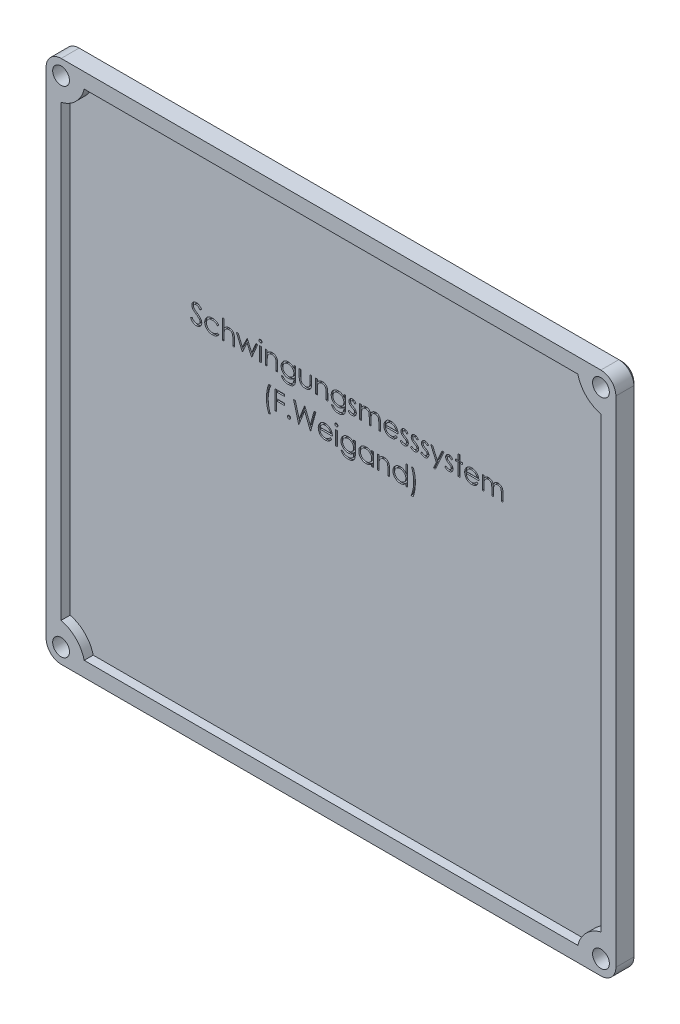
from build123d import *
from build123d.topology import SkipClean

# Parameters (mm, degrees)
SKIZZE1_W                       = 190
SKIZZE1_H                       = 175
SKIZZE1_W_2                     = 180
SKIZZE1_H_2                     = 165
AUFSATZ_LINEAR_AUSTRAGEN1_DEPTH = 3
SKIZZE1_2_W                     = 190
SKIZZE1_2_H                     = 175
AUFSATZ_LINEAR_AUSTRAGEN2_DEPTH = 4
SKIZZE2_R                       = 2.8
SCHNITT_LINEAR_AUSTRAGEN2_DEPTH = 130.345467644
VERRUNDUNG1_R                   = 5
FASE1_SIZE                      = 1
AUFSATZ_LINEAR_AUSTRAGEN3_DEPTH = 3
SKIZZE3_W                       = 0.569871795
SKIZZE3_H                       = 4.640384615
SKIZZE3_W_2                     = 0.569871794
SCHNITT_LINEAR_AUSTRAGEN3_DEPTH = 0.5


with BuildPart() as part:
    # Skizze1 → Aufsatz-Linear austragen1 (new body)
    with BuildSketch(Plane.XY):
        Rectangle(SKIZZE1_W, SKIZZE1_H)
        Rectangle(SKIZZE1_W_2, SKIZZE1_H_2, mode=Mode.SUBTRACT)
    extrude(amount=AUFSATZ_LINEAR_AUSTRAGEN1_DEPTH)

    # Skizze1<2> → Aufsatz-Linear austragen2 (add)
    with BuildSketch(Plane.XY):
        Rectangle(SKIZZE1_2_W, SKIZZE1_2_H)
    extrude(amount=-AUFSATZ_LINEAR_AUSTRAGEN2_DEPTH)

    # Skizze2 → Schnitt-Linear austragen2 (cut, through all)
    with BuildSketch(Plane.XY.offset(3)):
        with Locations((-90.025126266, 82.525126266)):
            Circle(SKIZZE2_R)
        with Locations(Location((90.025126266, 82.525126266, 0), (0, 0, 269.485839889))):
            Circle(SKIZZE2_R)
        with Locations((90.025126266, -82.525126266)):
            Circle(SKIZZE2_R)
        with Locations(Location((-90.025126266, -82.525126266, 0), (0, 0, 0.514160111))):
            Circle(SKIZZE2_R)
    extrude(amount=-SCHNITT_LINEAR_AUSTRAGEN2_DEPTH, mode=Mode.SUBTRACT)

    # Verrundung1
    verrundung1_edges = [part.edges().sort_by_distance(p)[0] for p in [
        (-95, 87.5, -0.5),
        (95, 87.5, -0.5),
        (95, -87.5, -0.5),
        (-95, -87.5, -0.5),
    ]]
    fillet(verrundung1_edges, radius=VERRUNDUNG1_R)

    # Fase1
    fase1_edges = [part.edges().sort_by_distance(p)[0] for p in [
        (0, -87.5, -4),
        (95, 0, -4),
        (-95, 0, -4),
        (0, 87.5, -4),
        (-93.535533906, 86.035533906, -4),
        (93.535533906, 86.035533906, -4),
        (93.535533906, -86.035533906, -4),
        (-93.535533906, -86.035533906, -4),
    ]]
    chamfer(fase1_edges, length=FASE1_SIZE)

    # Skizze2<5> → Aufsatz-Linear austragen3 (add)
    with SkipClean():  # the faces are left unmerged after this step: merging them gives an invalid solid
        with BuildSketch(Plane.XY.offset(3)):
            with BuildLine():
                Line((-92.5, 81.21554618), (-92.5, 74.5))
                ThreePointArc((-92.5, 74.5), (-85.075378798, 77.575378798), (-82, 85))
                Line((-82, 85), (-88.71554618, 85))
                ThreePointArc((-88.71554618, 85), (-88.045227279, 80.545227279), (-92.5, 81.21554618))
            make_face()
            with BuildLine():
                Line((92.5, 74.5), (92.5, 81.21554618))
                ThreePointArc((92.5, 81.21554618), (88.045227279, 80.545227279), (88.71554618, 85))
                Line((88.71554618, 85), (82, 85))
                ThreePointArc((82, 85), (85.075378798, 77.575378798), (92.5, 74.5))
            make_face()
            with BuildLine():
                Line((82, -85), (88.71554618, -85))
                ThreePointArc((88.71554618, -85), (88.045227279, -80.545227279), (92.5, -81.21554618))
                Line((92.5, -81.21554618), (92.5, -74.5))
                ThreePointArc((92.5, -74.5), (85.075378798, -77.575378798), (82, -85))
            make_face()
            with BuildLine():
                Line((-92.5, -74.5), (-92.5, -81.21554618))
                ThreePointArc((-92.5, -81.21554618), (-88.045227279, -80.545227279), (-88.71554618, -85))
                Line((-88.71554618, -85), (-82, -85))
                ThreePointArc((-82, -85), (-85.075378798, -77.575378798), (-92.5, -74.5))
            make_face()
        extrude(amount=-AUFSATZ_LINEAR_AUSTRAGEN3_DEPTH)

    # Skizze3 → Schnitt-Linear austragen3 (cut)
    # profile 1 of 34: a face of its own
    with SkipClean():  # the faces are left unmerged after this step: merging them gives an invalid solid
        with BuildSketch(Plane.XY):
            with BuildLine():
                Line((-49.837179487, 31.224969952), (-49.300380609, 31.546794872))
                add(Edge.make_bspline(
                    [(-49.300380609, 31.546794872), (-49.250454664, 31.463220916), (-49.154798481, 31.303096443), (-48.995229586, 31.086728284), (-48.829888448, 30.902828371), (-48.657550657, 30.752466525), (-48.479268151, 30.634086402), (-48.293877082, 30.550262353), (-48.102002197, 30.497981941), (-47.971421121, 30.491631784), (-47.906229968, 30.488461538)],
                    knots=[0, 0, 0, 0, 1.272034388, 2.437168799, 3.508375237, 4.49857839, 5.41946034, 6.295179144, 7.148887113, 8, 8, 8, 8], degree=3))
                add(Edge.make_bspline(
                    [(-47.906229968, 30.488461538), (-47.850555235, 30.490012159), (-47.740179947, 30.493086267), (-47.577688449, 30.522624293), (-47.419878608, 30.568003441), (-47.270002937, 30.632992846), (-47.130129464, 30.711621241), (-47.007471603, 30.806592163), (-46.901433655, 30.912920565), (-46.814694261, 31.031543381), (-46.748146197, 31.15911878), (-46.69699773, 31.290066577), (-46.668613097, 31.426443837), (-46.664337272, 31.518265676), (-46.662179487, 31.564603365)],
                    knots=[0, 0, 0, 0, 1.095163259, 2.171163733, 3.241058638, 4.321873601, 5.38011039, 6.391990106, 7.366004449, 8.327778327, 9.272591725, 10.192022065, 11.087607919, 12, 12, 12, 12], degree=3))
                add(Edge.make_bspline(
                    [(-46.662179487, 31.564603365), (-46.664854308, 31.617473193), (-46.670291828, 31.724949826), (-46.71625037, 31.883517768), (-46.78854829, 32.040440002), (-46.855246229, 32.137506584), (-46.889873798, 32.187900641)],
                    knots=[0, 0, 0, 0, 0.938893495, 1.908633276, 2.914225137, 4, 4, 4, 4], degree=3))
                add(Edge.make_bspline(
                    [(-46.889873798, 32.187900641), (-46.91830477, 32.224271307), (-46.977992038, 32.30062697), (-47.080603525, 32.414283326), (-47.201010618, 32.5315196), (-47.335092782, 32.65681246), (-47.487734243, 32.784334606), (-47.654154162, 32.920167053), (-47.838601449, 33.0591442), (-47.967959107, 33.152348712), (-48.034705529, 33.200440705)],
                    knots=[0, 0, 0, 0, 0.722233717, 1.516239348, 2.393582979, 3.351407094, 4.387010283, 5.505090956, 6.712668013, 8, 8, 8, 8], degree=3))
                add(Edge.make_bspline(
                    [(-48.034705529, 33.200440705), (-48.101514779, 33.248026857), (-48.229248978, 33.339007956), (-48.407880977, 33.474034871), (-48.567618789, 33.597485891), (-48.707752433, 33.71052317), (-48.828220273, 33.813162039), (-48.929971605, 33.904416871), (-49.010414415, 33.986755618), (-49.055146683, 34.040170623), (-49.075230369, 34.064152644)],
                    knots=[0, 0, 0, 0, 1.452282411, 2.77665338, 3.964542531, 5.026858415, 5.96415736, 6.766646006, 7.446254459, 8, 8, 8, 8], degree=3))
                add(Edge.make_bspline(
                    [(-49.075230369, 34.064152644), (-49.103301986, 34.101528811), (-49.15850859, 34.175034059), (-49.2313812, 34.289923444), (-49.293319395, 34.407531369), (-49.341873912, 34.528173866), (-49.382761052, 34.650157237), (-49.410261869, 34.775073068), (-49.427481975, 34.902360847), (-49.429245436, 34.988019627), (-49.430128205, 35.030899439)],
                    knots=[0, 0, 0, 0, 1.068054152, 2.10047183, 3.106115577, 4.101338837, 5.06977816, 6.043150881, 7.020423561, 8, 8, 8, 8], degree=3))
                add(Edge.make_bspline(
                    [(-49.430128205, 35.030899439), (-49.427760183, 35.09808203), (-49.423074754, 35.231011231), (-49.383449815, 35.425195738), (-49.320906137, 35.610591095), (-49.233285412, 35.785361843), (-49.120332786, 35.944957266), (-48.989620804, 36.091213164), (-48.83393425, 36.214164734), (-48.663114491, 36.321592326), (-48.476140787, 36.405677076), (-48.280214434, 36.469106283), (-48.075024032, 36.505045936), (-47.936044059, 36.510203524), (-47.86552484, 36.512820513)],
                    knots=[0, 0, 0, 0, 1.005424448, 1.989358655, 2.955360095, 3.929531133, 4.905563448, 5.876582895, 6.856512386, 7.866279853, 8.892233794, 9.918561126, 10.94386622, 12, 12, 12, 12], degree=3))
                add(Edge.make_bspline(
                    [(-47.86552484, 36.512820513), (-47.790696258, 36.510239598), (-47.641886091, 36.505106981), (-47.422993943, 36.460480032), (-47.212245214, 36.386637384), (-47.042712434, 36.302837962), (-46.91002871, 36.219142394), (-46.808841037, 36.142906427), (-46.706302234, 36.055140158), (-46.601585192, 35.955609812), (-46.496464281, 35.843402135), (-46.389378875, 35.719285599), (-46.280078558, 35.584018705), (-46.209764355, 35.487454254), (-46.173717949, 35.437950721)],
                    knots=[0, 0, 0, 0, 1.286793592, 2.559021753, 3.825965368, 5.121522368, 5.803751409, 6.523245864, 7.299691795, 8.125521123, 9.008227632, 9.944561021, 10.946284179, 12, 12, 12, 12], degree=3))
                Line((-46.173717949, 35.437950721), (-46.688892228, 35.047435897))
                add(Edge.make_bspline(
                    [(-46.688892228, 35.047435897), (-46.719999848, 35.087511093), (-46.779905851, 35.164686549), (-46.870855063, 35.272765936), (-46.95657761, 35.371492978), (-47.041033336, 35.457245424), (-47.119761781, 35.534719295), (-47.196174129, 35.601049139), (-47.269170738, 35.656884863), (-47.361185704, 35.716472464), (-47.476787851, 35.775539263), (-47.621902652, 35.825521162), (-47.773552037, 35.855556775), (-47.876838654, 35.859528042), (-47.929126603, 35.861538462)],
                    knots=[0, 0, 0, 0, 1.181633172, 2.275549214, 3.290209073, 4.226197932, 5.078386478, 5.862611352, 6.581680152, 7.217281963, 8.414376989, 9.595101626, 10.782541182, 12, 12, 12, 12], degree=3))
                add(Edge.make_bspline(
                    [(-47.929126603, 35.861538462), (-47.994724865, 35.859340092), (-48.121224934, 35.855100742), (-48.300821505, 35.808800198), (-48.46246334, 35.735898822), (-48.601351565, 35.633727362), (-48.716988652, 35.512676418), (-48.800637128, 35.373377638), (-48.850983855, 35.219558137), (-48.857127533, 35.112258274), (-48.86025641, 35.057612179)],
                    knots=[0, 0, 0, 0, 1.14458467, 2.207223713, 3.21896685, 4.227309161, 5.202851033, 6.127160689, 7.046193047, 8, 8, 8, 8], degree=3))
                add(Edge.make_bspline(
                    [(-48.86025641, 35.057612179), (-48.859543166, 35.02359164), (-48.858115512, 34.95549493), (-48.838204093, 34.854890208), (-48.812623882, 34.754539635), (-48.772087964, 34.654894377), (-48.716125771, 34.554211754), (-48.642637809, 34.450758031), (-48.550085085, 34.343621359), (-48.47918822, 34.27393941), (-48.441756811, 34.237149439)],
                    knots=[0, 0, 0, 0, 0.858281714, 1.717966888, 2.583508476, 3.4729293, 4.427298488, 5.488583878, 6.674047936, 8, 8, 8, 8], degree=3))
                add(Edge.make_bspline(
                    [(-48.441756811, 34.237149439), (-48.427856892, 34.224745121), (-48.394833868, 34.1952753), (-48.334461831, 34.147029305), (-48.25473704, 34.087515704), (-48.157741332, 34.013878716), (-48.041686262, 33.928459491), (-47.906559067, 33.832350224), (-47.753866, 33.722430891), (-47.645513381, 33.64558221), (-47.588221154, 33.604947917)],
                    knots=[0, 0, 0, 0, 0.420754252, 0.999615792, 1.744751191, 2.668019286, 3.750313428, 4.999500688, 6.413464383, 8, 8, 8, 8], degree=3))
                add(Edge.make_bspline(
                    [(-47.588221154, 33.604947917), (-47.519303854, 33.554798593), (-47.385855055, 33.457691378), (-47.195976302, 33.311794359), (-47.023811822, 33.169104836), (-46.868757153, 33.030534034), (-46.729280476, 32.897133065), (-46.606929183, 32.76729701), (-46.500456591, 32.641956042), (-46.385831438, 32.481260083), (-46.268705108, 32.283900116), (-46.168118373, 32.042095312), (-46.104693943, 31.799350559), (-46.096399908, 31.636197584), (-46.092307692, 31.555699119)],
                    knots=[0, 0, 0, 0, 1.163667725, 2.253281268, 3.268753668, 4.215851969, 5.092017293, 5.902905408, 6.650798638, 7.335211899, 8.59617414, 9.77448103, 10.901945474, 12, 12, 12, 12], degree=3))
                add(Edge.make_bspline(
                    [(-46.092307692, 31.555699119), (-46.093499929, 31.498769799), (-46.095861249, 31.386016689), (-46.123004621, 31.220453907), (-46.162773156, 31.059652186), (-46.222712138, 30.905599168), (-46.295869868, 30.755476527), (-46.38870006, 30.613222193), (-46.496301146, 30.475687727), (-46.619733833, 30.346540536), (-46.75479997, 30.227983866), (-46.897554674, 30.12252114), (-47.048231597, 30.034585753), (-47.206013343, 29.962829226), (-47.370936154, 29.906706987), (-47.542944562, 29.866043638), (-47.722322104, 29.841086848), (-47.844242978, 29.838496481), (-47.906229968, 29.837179487)],
                    knots=[0, 0, 0, 0, 0.983748083, 1.948392443, 2.894712957, 3.844097841, 4.80183111, 5.778335162, 6.776009319, 7.81870978, 8.863265674, 9.881300176, 10.883814829, 11.87499822, 12.874611388, 13.892143829, 14.928324115, 16, 16, 16, 16], degree=3))
                add(Edge.make_bspline(
                    [(-47.906229968, 29.837179487), (-47.954191233, 29.838106917), (-48.049509741, 29.839950096), (-48.190496943, 29.856244704), (-48.328635912, 29.879299021), (-48.462193253, 29.915900548), (-48.592889699, 29.960308778), (-48.720156825, 30.014988324), (-48.844056308, 30.080515246), (-48.965282494, 30.15543622), (-49.083527068, 30.242626699), (-49.19768096, 30.344178614), (-49.311489625, 30.457291173), (-49.421593902, 30.585036052), (-49.530220892, 30.725349431), (-49.635228863, 30.879544093), (-49.738791408, 31.046780149), (-49.8037709, 31.164463947), (-49.837179487, 31.224969952)],
                    knots=[0, 0, 0, 0, 0.915332311, 1.819136955, 2.706846663, 3.586547465, 4.459518054, 5.340707479, 6.227863349, 7.133153174, 8.059268498, 9.028702269, 10.047606654, 11.120612155, 12.245963614, 13.433783089, 14.680604001, 16, 16, 16, 16], degree=3))
            make_face()
        # profile 2 of 34: a face of its own
        with BuildSketch(Plane.XY):
            with BuildLine():
                Line((-40.393589744, 33.634204728), (-40.870602965, 33.337820513))
                add(Edge.make_bspline(
                    [(-40.870602965, 33.337820513), (-40.922908578, 33.402823456), (-41.025863296, 33.530770713), (-41.204641625, 33.695888735), (-41.395162334, 33.837706082), (-41.600681077, 33.953282887), (-41.8209096, 34.042584662), (-42.054979402, 34.105776606), (-42.302857104, 34.145154304), (-42.472792536, 34.149629851), (-42.559865785, 34.151923077)],
                    knots=[0, 0, 0, 0, 1.026593902, 2.0206758, 2.988051866, 3.946915611, 4.916868779, 5.907761954, 6.927957743, 8, 8, 8, 8], degree=3))
                add(Edge.make_bspline(
                    [(-42.559865785, 34.151923077), (-42.629459893, 34.150005663), (-42.766523595, 34.146229369), (-42.967739045, 34.122624617), (-43.159404457, 34.079731259), (-43.342721172, 34.023214523), (-43.51638536, 33.947467569), (-43.680852026, 33.855284154), (-43.837579987, 33.748150509), (-43.982027503, 33.624034234), (-44.11416013, 33.489053794), (-44.228639589, 33.344357804), (-44.328310882, 33.194280287), (-44.406517402, 33.035073555), (-44.47051664, 32.870379858), (-44.512620261, 32.697090434), (-44.540677637, 32.517425335), (-44.543887705, 32.394927776), (-44.545512821, 32.33291266)],
                    knots=[0, 0, 0, 0, 1.112346261, 2.190735716, 3.231507886, 4.247384806, 5.251966152, 6.253067467, 7.256802811, 8.280671706, 9.291813951, 10.270744147, 11.225547591, 12.165006084, 13.100104208, 14.043489273, 15.009504848, 16, 16, 16, 16], degree=3))
                add(Edge.make_bspline(
                    [(-44.545512821, 32.33291266), (-44.542284749, 32.25168852), (-44.5358721, 32.090334665), (-44.485613738, 31.85215868), (-44.403346027, 31.621882842), (-44.290755355, 31.401142079), (-44.148375412, 31.196864112), (-43.981148047, 31.013651273), (-43.788980567, 30.855053622), (-43.573566196, 30.723567755), (-43.339962861, 30.617864988), (-43.090697957, 30.542558827), (-42.827808355, 30.497106665), (-42.647818971, 30.491380883), (-42.556049679, 30.488461538)],
                    knots=[0, 0, 0, 0, 0.966302908, 1.919585723, 2.883856336, 3.870342332, 4.860282998, 5.839159637, 6.814385684, 7.815993281, 8.834850808, 9.858348828, 10.908058873, 12, 12, 12, 12], degree=3))
                add(Edge.make_bspline(
                    [(-42.556049679, 30.488461538), (-42.471948131, 30.490819198), (-42.30666627, 30.495452624), (-42.065062767, 30.534512314), (-41.835047786, 30.598454335), (-41.616629501, 30.687622215), (-41.410207029, 30.802879279), (-41.217114097, 30.945045203), (-41.033508495, 31.110030178), (-40.92556398, 31.237607069), (-40.870602965, 31.302564103)],
                    knots=[0, 0, 0, 0, 1.039848629, 2.043578496, 3.018386758, 3.987534228, 4.954977003, 5.934852016, 6.948509513, 8, 8, 8, 8], degree=3))
                Line((-40.870602965, 31.302564103), (-40.393589744, 30.989643429))
                add(Edge.make_bspline(
                    [(-40.393589744, 30.989643429), (-40.421870289, 30.948113111), (-40.478337513, 30.865190317), (-40.572730491, 30.748270277), (-40.6745479, 30.638829511), (-40.783392518, 30.537014717), (-40.897843122, 30.440389454), (-41.021809472, 30.353573026), (-41.151294339, 30.271685562), (-41.287817811, 30.198002208), (-41.429968363, 30.13176931), (-41.577545972, 30.074816757), (-41.729909347, 30.02588528), (-41.887237629, 29.986991808), (-42.049840988, 29.955947858), (-42.217298896, 29.935348999), (-42.38955368, 29.919972418), (-42.505980297, 29.919054631), (-42.564953926, 29.918589744)],
                    knots=[0, 0, 0, 0, 0.954134338, 1.905101784, 2.851144739, 3.791306361, 4.734911809, 5.6936923, 6.663572882, 7.643865596, 8.638447847, 9.640600242, 10.646758161, 11.676244097, 12.717260333, 13.78922464, 14.880174919, 16, 16, 16, 16], degree=3))
                add(Edge.make_bspline(
                    [(-42.564953926, 29.918589744), (-42.654962244, 29.92020678), (-42.831379199, 29.923376183), (-43.089592892, 29.958225845), (-43.336360545, 30.010763235), (-43.571597852, 30.086171723), (-43.795341434, 30.183244673), (-44.007382663, 30.301820789), (-44.207019439, 30.442884751), (-44.392277573, 30.603925775), (-44.562423911, 30.778533795), (-44.708521428, 30.966947218), (-44.835240705, 31.162238833), (-44.936999533, 31.36872183), (-45.018001814, 31.583651863), (-45.073346296, 31.808750727), (-45.109141677, 32.042162674), (-45.11328438, 32.201335189), (-45.115384615, 32.28203125)],
                    knots=[0, 0, 0, 0, 1.1129367, 2.181364009, 3.217532258, 4.231199276, 5.232079859, 6.230262199, 7.231623845, 8.250719726, 9.263571943, 10.242672461, 11.195837495, 12.138959767, 13.085126421, 14.0317438, 15.002148558, 16, 16, 16, 16], degree=3))
                add(Edge.make_bspline(
                    [(-45.115384615, 32.28203125), (-45.114584486, 32.336783553), (-45.112992897, 32.44569492), (-45.094737685, 32.607338826), (-45.071154741, 32.766830044), (-45.031193761, 32.922146907), (-44.985037187, 33.075645076), (-44.926117293, 33.225474417), (-44.857001363, 33.37233118), (-44.778529972, 33.515837061), (-44.690194678, 33.653631226), (-44.592438726, 33.783812874), (-44.488944002, 33.907945877), (-44.37486877, 34.0217447), (-44.255053969, 34.129760362), (-44.126109825, 34.229107244), (-43.988775923, 34.320077328), (-43.845114752, 34.404352742), (-43.695209918, 34.479390574), (-43.539967531, 34.544039448), (-43.380323035, 34.599289122), (-43.216021059, 34.64302959), (-43.048152145, 34.679709772), (-42.875393431, 34.702783579), (-42.698405828, 34.719087245), (-42.57856133, 34.720884825), (-42.517888622, 34.721794872)],
                    knots=[0, 0, 0, 0, 0.990994727, 1.971252077, 2.943264845, 3.907940874, 4.872158414, 5.844625996, 6.82015047, 7.809835459, 8.804511986, 9.781214284, 10.756496977, 11.728388426, 12.696359165, 13.676225489, 14.672885716, 15.677705647, 16.690706858, 17.706033469, 18.721040654, 19.747369689, 20.783475414, 21.830280724, 22.901553713, 24, 24, 24, 24], degree=3))
                add(Edge.make_bspline(
                    [(-42.517888622, 34.721794872), (-42.44190614, 34.720122298), (-42.290320973, 34.716785511), (-42.065457119, 34.688702813), (-41.843905267, 34.646363886), (-41.629552665, 34.583638895), (-41.424998275, 34.507686263), (-41.233526815, 34.422391766), (-41.059645484, 34.323341557), (-40.900119715, 34.214992207), (-40.754651162, 34.092780278), (-40.621746583, 33.955244798), (-40.498680591, 33.803101558), (-40.428909128, 33.690968302), (-40.393589744, 33.634204728)],
                    knots=[0, 0, 0, 0, 1.095225653, 2.184976855, 3.262915854, 4.344593502, 5.400796181, 6.407717688, 7.363229445, 8.282371371, 9.184954523, 10.097238608, 11.036792983, 12, 12, 12, 12], degree=3))
            make_face()
        # profile 3 of 34: a face of its own
        with BuildSketch(Plane.XY):
            with BuildLine():
                Line((-39.253846154, 36.512820513), (-38.683974359, 36.512820513))
                Line((-38.683974359, 36.512820513), (-38.683974359, 33.763952324))
                add(Edge.make_bspline(
                    [(-38.683974359, 33.763952324), (-38.62280154, 33.840413548), (-38.503694928, 33.989287471), (-38.303223402, 34.18352706), (-38.09735482, 34.351890273), (-37.878978665, 34.485912388), (-37.652101292, 34.591787831), (-37.415765823, 34.666876846), (-37.169928346, 34.713052408), (-37.002968431, 34.718855251), (-36.918389423, 34.721794872)],
                    knots=[0, 0, 0, 0, 1.125788106, 2.19196713, 3.20547328, 4.180437432, 5.132270164, 6.079753143, 7.027236121, 8, 8, 8, 8], degree=3))
                add(Edge.make_bspline(
                    [(-36.918389423, 34.721794872), (-36.832518568, 34.718628163), (-36.66444859, 34.712430149), (-36.419735079, 34.663420158), (-36.191206063, 34.579677377), (-35.979540891, 34.465074346), (-35.789358941, 34.322339359), (-35.62090294, 34.157545025), (-35.483306062, 33.96654806), (-35.389690521, 33.790097427), (-35.328778767, 33.633091402), (-35.290221882, 33.498405159), (-35.257529908, 33.348323973), (-35.229046102, 33.182925102), (-35.210062175, 33.001414577), (-35.194813797, 32.804611286), (-35.183970801, 32.592526515), (-35.183550605, 32.445714062), (-35.183333333, 32.369801683)],
                    knots=[0, 0, 0, 0, 1.235656852, 2.418478516, 3.575258207, 4.727955599, 5.870717718, 6.98870536, 8.107142894, 9.245821548, 9.854588956, 10.528768408, 11.260415777, 12.065282286, 12.943670737, 13.886611085, 14.907229059, 16, 16, 16, 16], degree=3))
                Line((-35.183333333, 32.369801683), (-35.183333333, 30))
                Line((-35.183333333, 30), (-35.753205128, 30))
                Line((-35.753205128, 30), (-35.753205128, 32.1828125))
                add(Edge.make_bspline(
                    [(-35.753205128, 32.1828125), (-35.753550393, 32.245990772), (-35.754210824, 32.366840054), (-35.756394035, 32.539861422), (-35.761267597, 32.696790123), (-35.769143096, 32.837123221), (-35.777425868, 32.961056359), (-35.7888256, 33.068409557), (-35.802088453, 33.159330264), (-35.8140061, 33.214057519), (-35.819350962, 33.238601763)],
                    knots=[0, 0, 0, 0, 1.430932559, 2.737130458, 3.918967929, 4.986496826, 5.920444988, 6.731744033, 7.431208747, 8, 8, 8, 8], degree=3))
                add(Edge.make_bspline(
                    [(-35.819350962, 33.238601763), (-35.840077806, 33.310618498), (-35.879925044, 33.449070253), (-35.97254066, 33.637143483), (-36.088217723, 33.797498655), (-36.229454898, 33.927971721), (-36.393753644, 34.030318371), (-36.582185293, 34.10119849), (-36.792976389, 34.145190785), (-36.941478345, 34.149616379), (-37.018880208, 34.151923077)],
                    knots=[0, 0, 0, 0, 1.090059168, 2.095632401, 3.037101401, 3.955032261, 4.878929692, 5.839099886, 6.873700383, 8, 8, 8, 8], degree=3))
                add(Edge.make_bspline(
                    [(-37.018880208, 34.151923077), (-37.064723168, 34.151059792), (-37.155445201, 34.149351374), (-37.289972067, 34.1321993), (-37.420471939, 34.104170911), (-37.548201604, 34.066244105), (-37.670453977, 34.014635775), (-37.79079251, 33.954891003), (-37.905807718, 33.881760311), (-38.017541985, 33.799707848), (-38.121532367, 33.708866998), (-38.218282991, 33.612987522), (-38.304531122, 33.510888659), (-38.382669852, 33.404208448), (-38.450121884, 33.291483623), (-38.509001048, 33.173801216), (-38.558958668, 33.051006467), (-38.583782981, 32.965780283), (-38.596203926, 32.923137019)],
                    knots=[0, 0, 0, 0, 1.024319606, 2.027102035, 3.025350316, 4.005802111, 5.00026367, 5.987881639, 7.005602596, 8.042517216, 9.083927026, 10.089214625, 11.084353441, 12.06828073, 13.041928858, 14.016821737, 15.00770877, 16, 16, 16, 16], degree=3))
                add(Edge.make_bspline(
                    [(-38.596203926, 32.923137019), (-38.603351173, 32.892256151), (-38.618925903, 32.824962939), (-38.635825672, 32.713975237), (-38.650952817, 32.585004247), (-38.6637409, 32.438245587), (-38.671584214, 32.273161476), (-38.680035594, 32.09087845), (-38.683181591, 31.890254698), (-38.683702205, 31.750744278), (-38.683974359, 31.677814503)],
                    knots=[0, 0, 0, 0, 0.607992626, 1.324890765, 2.152360218, 3.099583803, 4.150613268, 5.323148443, 6.60066238, 8, 8, 8, 8], degree=3))
                Line((-38.683974359, 31.677814503), (-38.683974359, 30))
                Line((-38.683974359, 30), (-39.253846154, 30))
                Line((-39.253846154, 30), (-39.253846154, 36.512820513))
            make_face()
        # profile 4 of 34: a face of its own
        with BuildSketch(Plane.XY):
            Polygon((-34.532051282, 34.640384615), (-33.920202324, 34.640384615), (-32.5375, 31.302564103), (-31.02250601, 34.640384615), (-30.92583133, 34.640384615), (-29.443910256, 31.302564103), (-28.04848758, 34.640384615), (-27.449358974, 34.640384615), (-29.38921274, 30), (-29.507512019, 30), (-30.990705128, 33.337820513), (-32.504427083, 30), (-32.61000601, 30), align=None)
        # profile 5 of 34: a face of its own
        with BuildSketch(Plane.XY):
            with BuildLine():
                add(Edge.make_bspline(
                    [(-26.515685096, 36.594230769), (-26.48032228, 36.592590378), (-26.411075095, 36.589378178), (-26.310938738, 36.561870927), (-26.219758159, 36.515244355), (-26.138881415, 36.452688362), (-26.069481564, 36.379120086), (-26.020893703, 36.293375187), (-25.989665499, 36.200740228), (-25.985894406, 36.13612428), (-25.983974359, 36.10322516)],
                    knots=[0, 0, 0, 0, 1.055194115, 2.066272739, 3.074728998, 4.095836921, 5.109056067, 6.073838105, 7.019297344, 8, 8, 8, 8], degree=3))
                add(Edge.make_bspline(
                    [(-25.983974359, 36.10322516), (-25.985937706, 36.071180061), (-25.989819011, 36.007830692), (-26.020869583, 35.916801678), (-26.069895643, 35.832248193), (-26.138836913, 35.758822761), (-26.219769951, 35.696301351), (-26.310935606, 35.64966561), (-26.411075919, 35.622160789), (-26.480322559, 35.618948254), (-26.515685096, 35.617307692)],
                    knots=[0, 0, 0, 0, 0.96129708, 1.900370562, 2.859976407, 3.87933698, 4.906634145, 5.921202961, 6.938410037, 8, 8, 8, 8], degree=3))
                add(Edge.make_bspline(
                    [(-26.515685096, 35.617307692), (-26.550643253, 35.618885613), (-26.618684737, 35.62195683), (-26.717321722, 35.650205291), (-26.807724838, 35.696317309), (-26.888759316, 35.758413388), (-26.956305523, 35.83269913), (-27.005469628, 35.916750078), (-27.036448488, 36.00784383), (-27.040339457, 36.071184474), (-27.042307692, 36.10322516)],
                    knots=[0, 0, 0, 0, 1.054934014, 2.053291228, 3.073705704, 4.106921865, 5.123545215, 6.088680038, 7.033164197, 8, 8, 8, 8], degree=3))
                add(Edge.make_bspline(
                    [(-27.042307692, 36.10322516), (-27.040382578, 36.136119702), (-27.036601532, 36.200726657), (-27.005446407, 36.293427645), (-26.956715042, 36.378665512), (-26.888714591, 36.45309749), (-26.807736741, 36.515228493), (-26.717318646, 36.561331274), (-26.618685549, 36.589582132), (-26.550643528, 36.592653018), (-26.515685096, 36.594230769)],
                    knots=[0, 0, 0, 0, 0.98631895, 1.937192651, 2.907499808, 3.917963147, 4.944918757, 5.95915025, 6.951458133, 8, 8, 8, 8], degree=3))
            make_face()
        # profile 6 of 34: a face of its own
        with BuildSketch(Plane.XY):
            with Locations((-26.513141026, 32.320192308)):
                Rectangle(SKIZZE3_W, SKIZZE3_H)
        # profile 7 of 34: a face of its own
        with BuildSketch(Plane.XY):
            with BuildLine():
                Line((-24.844230769, 34.640384615), (-24.274358974, 34.640384615))
                Line((-24.274358974, 34.640384615), (-24.274358974, 33.803385417))
                add(Edge.make_bspline(
                    [(-24.274358974, 33.803385417), (-24.213512122, 33.879300071), (-24.095436682, 34.026615106), (-23.898796535, 34.22023672), (-23.690981173, 34.379794485), (-23.473263252, 34.506982797), (-23.24534722, 34.602861676), (-23.008622358, 34.67210558), (-22.761671392, 34.713625197), (-22.593733056, 34.719050329), (-22.508774038, 34.721794872)],
                    knots=[0, 0, 0, 0, 1.12780773, 2.188550248, 3.19190651, 4.159438251, 5.104880172, 6.052711206, 7.014878035, 8, 8, 8, 8], degree=3))
                add(Edge.make_bspline(
                    [(-22.508774038, 34.721794872), (-22.422902745, 34.718628589), (-22.254831911, 34.712431409), (-22.010124571, 34.663415412), (-21.781572842, 34.579694735), (-21.569991648, 34.465009979), (-21.379260847, 34.322395377), (-21.211757188, 34.156247116), (-21.073212439, 33.965137365), (-20.980325795, 33.787839638), (-20.919137834, 33.630561397), (-20.880616307, 33.495856579), (-20.847902955, 33.345782219), (-20.819542498, 33.180791822), (-20.800352595, 32.999729391), (-20.785217295, 32.80333715), (-20.774370235, 32.591678713), (-20.773939874, 32.445290118), (-20.773717949, 32.369801683)],
                    knots=[0, 0, 0, 0, 1.235846778, 2.418850247, 3.575807741, 4.728682307, 5.871620074, 6.994088408, 8.11269785, 9.256955736, 9.865816715, 10.540099792, 11.271859618, 12.076849838, 12.949306005, 13.892391288, 14.913166135, 16, 16, 16, 16], degree=3))
                Line((-20.773717949, 32.369801683), (-20.773717949, 30))
                Line((-20.773717949, 30), (-21.343589744, 30))
                Line((-21.343589744, 30), (-21.343589744, 32.1828125))
                add(Edge.make_bspline(
                    [(-21.343589744, 32.1828125), (-21.343940278, 32.245990364), (-21.344610791, 32.366838867), (-21.346725607, 32.539865523), (-21.351823399, 32.696776887), (-21.358986767, 32.837197825), (-21.369471579, 32.9609935), (-21.380398353, 33.068416045), (-21.393760526, 33.159329072), (-21.405667525, 33.21405715), (-21.411007612, 33.238601763)],
                    knots=[0, 0, 0, 0, 1.430800155, 2.736877192, 3.918605307, 4.986035426, 5.920637409, 6.731861385, 7.431261377, 8, 8, 8, 8], degree=3))
                add(Edge.make_bspline(
                    [(-21.411007612, 33.238601763), (-21.430285362, 33.310649198), (-21.467389067, 33.449318221), (-21.55907215, 33.637413118), (-21.674849307, 33.79742983), (-21.816178262, 33.928379025), (-21.981693871, 34.030288971), (-22.17093683, 34.100998861), (-22.382080935, 34.145224378), (-22.530588172, 34.149627889), (-22.607992788, 34.151923077)],
                    knots=[0, 0, 0, 0, 1.084156227, 2.086665306, 3.027808233, 3.945421172, 4.874247719, 5.839848303, 6.874090471, 8, 8, 8, 8], degree=3))
                add(Edge.make_bspline(
                    [(-22.607992788, 34.151923077), (-22.653835586, 34.151059468), (-22.744557297, 34.14935041), (-22.879086532, 34.132203055), (-23.009577532, 34.104156999), (-23.137339911, 34.066295329), (-23.259818337, 34.014293783), (-23.380947837, 33.955276211), (-23.496167252, 33.88171017), (-23.607933415, 33.799721471), (-23.711915223, 33.70886348), (-23.808668066, 33.612988441), (-23.894915617, 33.510888417), (-23.973054499, 33.404208512), (-24.040506491, 33.291483606), (-24.099385665, 33.173801221), (-24.149343283, 33.051006465), (-24.174167596, 32.965780283), (-24.186588542, 32.923137019)],
                    knots=[0, 0, 0, 0, 1.023777757, 2.026029729, 3.023749952, 4.003683103, 4.997618607, 5.993177895, 7.010360494, 8.046726602, 9.087585522, 10.09234134, 11.086953743, 12.070360549, 13.043493632, 14.017870808, 15.008233677, 16, 16, 16, 16], degree=3))
                add(Edge.make_bspline(
                    [(-24.186588542, 32.923137019), (-24.19373619, 32.891831151), (-24.209296246, 32.823679913), (-24.226102301, 32.711839324), (-24.241356045, 32.582462655), (-24.254123098, 32.435700879), (-24.261934354, 32.271040163), (-24.270451331, 32.089183715), (-24.273552056, 31.889406386), (-24.27408247, 31.750320172), (-24.274358974, 31.677814503)],
                    knots=[0, 0, 0, 0, 0.615963638, 1.340920617, 2.168419149, 3.115676021, 4.16674242, 5.331190069, 6.6087489, 8, 8, 8, 8], degree=3))
                Line((-24.274358974, 31.677814503), (-24.274358974, 30))
                Line((-24.274358974, 30), (-24.844230769, 30))
                Line((-24.844230769, 30), (-24.844230769, 34.640384615))
            make_face()
        # profile 8 of 34: a face of its own
        with BuildSketch(Plane.XY):
            with BuildLine():
                Line((-15.400641026, 34.640384615), (-14.830769231, 34.640384615))
                Line((-14.830769231, 34.640384615), (-14.830769231, 30.957842548))
                add(Edge.make_bspline(
                    [(-14.830769231, 30.957842548), (-14.831271865, 30.879397198), (-14.832242071, 30.727978776), (-14.839228833, 30.509033897), (-14.853962061, 30.306802571), (-14.87066924, 30.120362473), (-14.894702569, 29.950577787), (-14.924051121, 29.796941888), (-14.957135853, 29.659307339), (-14.986201104, 29.574535127), (-14.99994992, 29.534435096)],
                    knots=[0, 0, 0, 0, 1.307562039, 2.523909702, 3.650326591, 4.686913197, 5.643429486, 6.506965704, 7.293745905, 8, 8, 8, 8], degree=3))
                add(Edge.make_bspline(
                    [(-14.99994992, 29.534435096), (-15.020250396, 29.48231081), (-15.060244377, 29.37962072), (-15.135148312, 29.234052738), (-15.219029823, 29.096990002), (-15.314836356, 28.96919634), (-15.422134672, 28.851313285), (-15.538396807, 28.740779743), (-15.665887012, 28.639934183), (-15.80453239, 28.550516571), (-15.951136896, 28.469985773), (-16.105616252, 28.400232716), (-16.267099362, 28.339478014), (-16.43710318, 28.293970656), (-16.612962319, 28.254537663), (-16.796744801, 28.228875161), (-16.987376876, 28.211408927), (-17.116999208, 28.20979379), (-17.18276242, 28.208974359)],
                    knots=[0, 0, 0, 0, 0.981931301, 1.934503488, 2.87077864, 3.801706999, 4.735015492, 5.667491629, 6.616593066, 7.585388521, 8.561939025, 9.551802639, 10.560317337, 11.588439944, 12.640189604, 13.723962949, 14.845264515, 16, 16, 16, 16], degree=3))
                add(Edge.make_bspline(
                    [(-17.18276242, 28.208974359), (-17.278710438, 28.210528269), (-17.466122697, 28.213563473), (-17.739363184, 28.248925561), (-17.998869033, 28.298917067), (-18.241211261, 28.374582628), (-18.464858437, 28.46717831), (-18.668283183, 28.573486296), (-18.849659335, 28.695386899), (-19.013169427, 28.834180846), (-19.160746312, 28.999214954), (-19.299588681, 29.193704286), (-19.433230676, 29.420611356), (-19.511550919, 29.587149565), (-19.552564103, 29.674358974)],
                    knots=[0, 0, 0, 0, 1.157897085, 2.2616841, 3.32207898, 4.345638746, 5.321241055, 6.241986252, 7.112515963, 7.955008012, 8.825025602, 9.77857164, 10.836726669, 12, 12, 12, 12], degree=3))
                Line((-19.552564103, 29.674358974), (-18.982692308, 29.674358974))
                add(Edge.make_bspline(
                    [(-18.982692308, 29.674358974), (-18.936859442, 29.601595457), (-18.847261834, 29.45935174), (-18.679715304, 29.275177872), (-18.496098112, 29.117782481), (-18.290213544, 28.990944363), (-18.061204939, 28.895313741), (-17.808934523, 28.827141418), (-17.531349495, 28.786326762), (-17.33809502, 28.7814077), (-17.237459936, 28.778846154)],
                    knots=[0, 0, 0, 0, 0.997731894, 1.950442991, 2.880492273, 3.800895997, 4.748200782, 5.754801363, 6.83083817, 8, 8, 8, 8], degree=3))
                add(Edge.make_bspline(
                    [(-17.237459936, 28.778846154), (-17.138097149, 28.781440852), (-16.946535642, 28.786443171), (-16.671070521, 28.827159633), (-16.419619705, 28.895328577), (-16.193631912, 28.990775221), (-15.995773589, 29.107706673), (-15.825208977, 29.238335379), (-15.687060778, 29.385620913), (-15.594145825, 29.521296476), (-15.536388733, 29.642171682), (-15.499609103, 29.746225678), (-15.469720616, 29.863887327), (-15.444720053, 29.994762163), (-15.424089968, 30.139037169), (-15.411021881, 30.29704223), (-15.401577052, 30.468418247), (-15.400960249, 30.587241512), (-15.400641026, 30.648737981)],
                    knots=[0, 0, 0, 0, 1.570740765, 3.028230971, 4.391408896, 5.680370741, 6.894727393, 8.017376726, 9.065722033, 10.075533815, 10.603371122, 11.180248986, 11.817768598, 12.521299649, 13.286540596, 14.121245857, 15.027658897, 16, 16, 16, 16], degree=3))
                Line((-15.400641026, 30.648737981), (-15.400641026, 30.889152644))
                add(Edge.make_bspline(
                    [(-15.400641026, 30.889152644), (-15.458482481, 30.820315375), (-15.57314798, 30.683851662), (-15.771172416, 30.505032692), (-15.987465963, 30.351024999), (-16.22166039, 30.224716905), (-16.468019058, 30.123694892), (-16.723873676, 30.053041234), (-16.98693069, 30.007393987), (-17.165188162, 30.002482142), (-17.255268429, 30)],
                    knots=[0, 0, 0, 0, 1.012485704, 2.007162095, 2.997754123, 3.998611389, 4.999708251, 5.992315798, 6.98544096, 8, 8, 8, 8], degree=3))
                add(Edge.make_bspline(
                    [(-17.255268429, 30), (-17.308311375, 30.000934405), (-17.413769558, 30.002792158), (-17.570441743, 30.01904594), (-17.724801967, 30.042629372), (-17.876490229, 30.077248554), (-18.025725413, 30.121683544), (-18.172260901, 30.177231056), (-18.317283156, 30.24003277), (-18.458156088, 30.314006285), (-18.59347664, 30.39630647), (-18.722224133, 30.485458458), (-18.843724197, 30.580995638), (-18.956820399, 30.683860086), (-19.061364388, 30.793902924), (-19.158762263, 30.909951084), (-19.24740345, 31.033625029), (-19.329106885, 31.162669652), (-19.399968441, 31.297944471), (-19.462170087, 31.436516159), (-19.516252864, 31.578088419), (-19.559370093, 31.723135232), (-19.592301399, 31.871565156), (-19.616812811, 32.023135028), (-19.630715558, 32.178311588), (-19.632883492, 32.282853179), (-19.633974359, 32.335456731)],
                    knots=[0, 0, 0, 0, 1.028754217, 2.045334182, 3.052854819, 4.056607503, 5.061168794, 6.071104265, 7.095078842, 8.125279047, 9.155117945, 10.165957491, 11.161587969, 12.151493252, 13.128948131, 14.104219989, 15.088194871, 16.07871515, 17.064853787, 18.047899887, 19.02414258, 20.002704429, 20.980574569, 21.971845993, 22.979467364, 24, 24, 24, 24], degree=3))
                add(Edge.make_bspline(
                    [(-19.633974359, 32.335456731), (-19.633032443, 32.388076634), (-19.631152259, 32.493112634), (-19.614912625, 32.648922377), (-19.591747482, 32.80264578), (-19.555084815, 32.952698352), (-19.51095681, 33.100788973), (-19.456304043, 33.245823801), (-19.390592865, 33.38784701), (-19.316189462, 33.526963775), (-19.232579751, 33.661307304), (-19.140899393, 33.788899933), (-19.041037707, 33.90880276), (-18.934372374, 34.022225411), (-18.819600992, 34.128073548), (-18.696782934, 34.22609027), (-18.567128852, 34.317918575), (-18.430236912, 34.401577716), (-18.288219365, 34.475568363), (-18.144684295, 34.543082646), (-17.997730354, 34.596665977), (-17.850097319, 34.643879314), (-17.699185188, 34.677326025), (-17.546844345, 34.703129235), (-17.392553246, 34.718849515), (-17.289224422, 34.720811819), (-17.237459936, 34.721794872)],
                    knots=[0, 0, 0, 0, 1.008818848, 2.013730394, 3.001654427, 3.987803273, 4.973046549, 5.963777569, 6.957074694, 7.972068341, 8.987420212, 9.989399531, 10.982630087, 11.977756091, 12.973280677, 13.973972381, 14.989194003, 16.018387222, 17.047741039, 18.059210846, 19.057554164, 20.045176975, 21.029480261, 22.018708529, 23.007435371, 24, 24, 24, 24], degree=3))
                add(Edge.make_bspline(
                    [(-17.237459936, 34.721794872), (-17.152096089, 34.719333479), (-16.983528722, 34.714472984), (-16.735459618, 34.67633462), (-16.496078697, 34.615530625), (-16.264035154, 34.528416552), (-16.037438759, 34.409490054), (-15.817036327, 34.252839277), (-15.602190183, 34.057059089), (-15.469606119, 33.906921749), (-15.400641026, 33.828826122)],
                    knots=[0, 0, 0, 0, 0.96728863, 1.910097829, 2.838038873, 3.762875196, 4.71315279, 5.730631239, 6.819562287, 8, 8, 8, 8], degree=3))
                Line((-15.400641026, 33.828826122), (-15.400641026, 34.640384615))
            make_face()
            with BuildLine():
                add(Edge.make_bspline(
                    [(-17.191666667, 34.151923077), (-17.274998087, 34.149090858), (-17.439976628, 34.143483665), (-17.681799764, 34.095614257), (-17.915256486, 34.020600981), (-18.135883477, 33.913299379), (-18.342543519, 33.782499833), (-18.525922122, 33.624039597), (-18.686313898, 33.443071497), (-18.821991515, 33.241231763), (-18.929998423, 33.023477063), (-19.006458627, 32.793950446), (-19.055897955, 32.556360673), (-19.061354695, 32.394213236), (-19.064102564, 32.312560096)],
                    knots=[0, 0, 0, 0, 1.026226791, 2.031711442, 3.026614839, 4.04107745, 5.047145931, 6.032893242, 7.017642609, 8.019221815, 9.021877557, 10.003543541, 10.994637589, 12, 12, 12, 12], degree=3))
                add(Edge.make_bspline(
                    [(-19.064102564, 32.312560096), (-19.062785834, 32.250995445), (-19.06019621, 32.129915778), (-19.035297719, 31.952228455), (-18.995055111, 31.782991314), (-18.938019037, 31.622194121), (-18.867347719, 31.468914564), (-18.77846156, 31.324208524), (-18.673866226, 31.187947129), (-18.554380384, 31.061138206), (-18.422706091, 30.945639021), (-18.279886973, 30.844151433), (-18.126116734, 30.761146553), (-17.965177235, 30.689408176), (-17.793163435, 30.637013296), (-17.612552951, 30.597028654), (-17.422068016, 30.574152765), (-17.292216431, 30.571317404), (-17.226011619, 30.569871795)],
                    knots=[0, 0, 0, 0, 1.039728707, 2.044842319, 3.024901384, 3.974314358, 4.923051295, 5.871625912, 6.837440708, 7.820715446, 8.810779094, 9.792721783, 10.773906224, 11.758876063, 12.764959493, 13.806266761, 14.881525401, 16, 16, 16, 16], degree=3))
                add(Edge.make_bspline(
                    [(-17.226011619, 30.569871795), (-17.1589488, 30.571264457), (-17.027808169, 30.573987793), (-16.836272328, 30.597398426), (-16.654784356, 30.63517544), (-16.483510664, 30.688811215), (-16.321804574, 30.757249248), (-16.17148263, 30.843857111), (-16.029321646, 30.942489724), (-15.899860731, 31.057537235), (-15.782795459, 31.184328583), (-15.680776782, 31.32229575), (-15.593846282, 31.469362692), (-15.521859652, 31.62551283), (-15.466902753, 31.791959671), (-15.430038454, 31.968287116), (-15.404263359, 32.1536504), (-15.401866825, 32.280666032), (-15.400641026, 32.345633013)],
                    knots=[0, 0, 0, 0, 1.121943988, 2.193949579, 3.223793937, 4.220241907, 5.192961521, 6.155822191, 7.11847367, 8.083710714, 9.04790392, 10.001595906, 10.949595423, 11.902125208, 12.873731292, 13.87582262, 14.913508608, 16, 16, 16, 16], degree=3))
                add(Edge.make_bspline(
                    [(-15.400641026, 32.345633013), (-15.403071385, 32.430211119), (-15.407819453, 32.595447018), (-15.452627154, 32.836215012), (-15.524872392, 33.062581034), (-15.626194357, 33.273829162), (-15.753161716, 33.467721059), (-15.906089398, 33.640665748), (-16.082340054, 33.792885874), (-16.281407293, 33.919701168), (-16.495579086, 34.022145599), (-16.719681828, 34.099001957), (-16.953382808, 34.1425345), (-17.111781579, 34.14877554), (-17.191666667, 34.151923077)],
                    knots=[0, 0, 0, 0, 1.070913519, 2.092188694, 3.091357305, 4.074328408, 5.051968682, 6.018948707, 6.99050112, 7.9935919, 9.000589572, 9.992915277, 10.987769056, 12, 12, 12, 12], degree=3))
            make_face(mode=Mode.SUBTRACT)
        # profile 9 of 34: a face of its own
        with BuildSketch(Plane.XY):
            with BuildLine():
                Line((-13.609615385, 34.640384615), (-13.03974359, 34.640384615))
                Line((-13.03974359, 34.640384615), (-13.03974359, 32.488100962))
                add(Edge.make_bspline(
                    [(-13.03974359, 32.488100962), (-13.039486134, 32.424922545), (-13.038993632, 32.304065194), (-13.03565364, 32.130156498), (-13.027797613, 31.971557605), (-13.017975388, 31.828176897), (-13.005344084, 31.700038629), (-12.990315701, 31.587590367), (-12.973518279, 31.489556919), (-12.957075927, 31.430513974), (-12.949429087, 31.403054888)],
                    knots=[0, 0, 0, 0, 1.388932606, 2.656963016, 3.823490214, 4.879454478, 5.816252168, 6.653371382, 7.373723809, 8, 8, 8, 8], degree=3))
                add(Edge.make_bspline(
                    [(-12.949429087, 31.403054888), (-12.937161875, 31.368541965), (-12.912882485, 31.300233634), (-12.86884345, 31.201556439), (-12.814363468, 31.110161284), (-12.754746352, 31.022523894), (-12.685985998, 30.94124029), (-12.608952386, 30.866447733), (-12.526224156, 30.795320311), (-12.403297185, 30.711165045), (-12.235186803, 30.620967232), (-12.014473947, 30.543141961), (-11.775161994, 30.496631259), (-11.609763146, 30.491235111), (-11.524749599, 30.488461538)],
                    knots=[0, 0, 0, 0, 0.725840625, 1.436591201, 2.137033971, 2.831655856, 3.53531722, 4.242432219, 4.957935707, 5.694543706, 7.190802206, 8.724350549, 10.316345118, 12, 12, 12, 12], degree=3))
                add(Edge.make_bspline(
                    [(-11.524749599, 30.488461538), (-11.43974395, 30.491294089), (-11.275273746, 30.496774552), (-11.038591159, 30.541738972), (-10.822235021, 30.616860722), (-10.628376866, 30.721739883), (-10.457895985, 30.850086197), (-10.315829397, 31.000687893), (-10.198613378, 31.168780352), (-10.147433429, 31.294191544), (-10.121694712, 31.357261619)],
                    knots=[0, 0, 0, 0, 1.157059328, 2.238695713, 3.266970494, 4.264342957, 5.228770407, 6.160125903, 7.074715775, 8, 8, 8, 8], degree=3))
                add(Edge.make_bspline(
                    [(-10.121694712, 31.357261619), (-10.11408518, 31.382600475), (-10.097262364, 31.438618497), (-10.079187812, 31.533650326), (-10.062905574, 31.646978966), (-10.049002383, 31.779346002), (-10.039087017, 31.930405521), (-10.033742083, 32.100110317), (-10.027703641, 32.287927642), (-10.02761199, 32.419404862), (-10.027564103, 32.488100962)],
                    knots=[0, 0, 0, 0, 0.557542046, 1.232589297, 2.036731608, 2.971723315, 4.038036528, 5.22795436, 6.551621927, 8, 8, 8, 8], degree=3))
                Line((-10.027564103, 32.488100962), (-10.027564103, 34.640384615))
                Line((-10.027564103, 34.640384615), (-9.457692308, 34.640384615))
                Line((-9.457692308, 34.640384615), (-9.457692308, 32.38125))
                add(Edge.make_bspline(
                    [(-9.457692308, 32.38125), (-9.458493668, 32.304492703), (-9.460048417, 32.155573048), (-9.470040312, 31.939157588), (-9.487184609, 31.737477515), (-9.513206338, 31.550426074), (-9.54380549, 31.378146071), (-9.583277586, 31.220416705), (-9.630409531, 31.077723943), (-9.683578108, 30.947563862), (-9.746392068, 30.829550211), (-9.813206805, 30.717543801), (-9.890358891, 30.614323761), (-9.971584888, 30.514751884), (-10.06193932, 30.423780827), (-10.159729065, 30.339323149), (-10.263577726, 30.260087792), (-10.375789843, 30.189165042), (-10.494727271, 30.125271985), (-10.62053684, 30.068637101), (-10.754759508, 30.023819568), (-10.895663536, 29.985155932), (-11.043939264, 29.954831109), (-11.199443748, 29.933446909), (-11.362124609, 29.920338095), (-11.472994629, 29.919182313), (-11.52983774, 29.918589744)],
                    knots=[0, 0, 0, 0, 1.493040784, 2.896703357, 4.213163133, 5.428574705, 6.569057535, 7.615249723, 8.588095153, 9.490268104, 10.346124644, 11.18633936, 12.024365274, 12.850166724, 13.684164916, 14.514361689, 15.362232829, 16.222528818, 17.093394965, 17.986930858, 18.902426812, 19.842810585, 20.827885679, 21.843828298, 22.894529745, 24, 24, 24, 24], degree=3))
                add(Edge.make_bspline(
                    [(-11.52983774, 29.918589744), (-11.586255702, 29.919206069), (-11.697122248, 29.920417207), (-11.859811505, 29.933374487), (-12.015746834, 29.954797882), (-12.164373842, 29.985378062), (-12.305841678, 30.023548946), (-12.44072337, 30.068912503), (-12.567439549, 30.125301377), (-12.687512613, 30.18876066), (-12.80000266, 30.260543374), (-12.905428223, 30.339225389), (-13.003647941, 30.424689246), (-13.094683479, 30.516578023), (-13.177257022, 30.616031607), (-13.252397555, 30.722249981), (-13.321261863, 30.834180685), (-13.38358764, 30.954038136), (-13.437130396, 31.085704497), (-13.484402057, 31.231386373), (-13.523065643, 31.392680939), (-13.554529836, 31.569450295), (-13.579841735, 31.760848442), (-13.597415165, 31.967982567), (-13.607241029, 32.190348123), (-13.608806869, 32.343927209), (-13.609615385, 32.423227163)],
                    knots=[0, 0, 0, 0, 1.083640291, 2.129454052, 3.13281866, 4.105697902, 5.042300162, 5.946461698, 6.836384745, 7.703652036, 8.553297018, 9.397182691, 10.228592656, 11.052265423, 11.879314572, 12.708807002, 13.549817954, 14.402308542, 15.300838682, 16.27712199, 17.341985831, 18.484375296, 19.725102775, 21.0496083, 22.476576903, 24, 24, 24, 24], degree=3))
                Line((-13.609615385, 32.423227163), (-13.609615385, 34.640384615))
            make_face()
        # profile 10 of 34: a face of its own
        with BuildSketch(Plane.XY):
            with BuildLine():
                Line((-8.155128205, 34.640384615), (-7.58525641, 34.640384615))
                Line((-7.58525641, 34.640384615), (-7.58525641, 33.803385417))
                add(Edge.make_bspline(
                    [(-7.58525641, 33.803385417), (-7.524409558, 33.879300071), (-7.406334118, 34.026615106), (-7.209693971, 34.22023672), (-7.001878609, 34.379794485), (-6.784160688, 34.506982797), (-6.556244655, 34.602861676), (-6.319519794, 34.67210558), (-6.072568827, 34.713625197), (-5.904630492, 34.719050329), (-5.819671474, 34.721794872)],
                    knots=[0, 0, 0, 0, 1.12780773, 2.188550248, 3.19190651, 4.159438251, 5.104880172, 6.052711206, 7.014878035, 8, 8, 8, 8], degree=3))
                add(Edge.make_bspline(
                    [(-5.819671474, 34.721794872), (-5.733800181, 34.718628589), (-5.565729347, 34.712431409), (-5.321022007, 34.663415412), (-5.092470278, 34.579694735), (-4.880889084, 34.465009979), (-4.690158283, 34.322395377), (-4.522654624, 34.156247116), (-4.384109875, 33.965137365), (-4.291223231, 33.787839638), (-4.23003527, 33.630561397), (-4.191513743, 33.495856579), (-4.158800391, 33.345782219), (-4.130439934, 33.180791822), (-4.111250031, 32.999729391), (-4.096114731, 32.80333715), (-4.085267671, 32.591678713), (-4.08483731, 32.445290118), (-4.084615385, 32.369801683)],
                    knots=[0, 0, 0, 0, 1.235846778, 2.418850247, 3.575807741, 4.728682307, 5.871620074, 6.994088408, 8.11269785, 9.256955736, 9.865816715, 10.540099792, 11.271859618, 12.076849838, 12.949306005, 13.892391288, 14.913166135, 16, 16, 16, 16], degree=3))
                Line((-4.084615385, 32.369801683), (-4.084615385, 30))
                Line((-4.084615385, 30), (-4.654487179, 30))
                Line((-4.654487179, 30), (-4.654487179, 32.1828125))
                add(Edge.make_bspline(
                    [(-4.654487179, 32.1828125), (-4.654837714, 32.245990364), (-4.655508227, 32.366838867), (-4.657623043, 32.539865523), (-4.662720835, 32.696776887), (-4.669884203, 32.837197825), (-4.680369015, 32.9609935), (-4.691295789, 33.068416045), (-4.704657962, 33.159329072), (-4.716564961, 33.21405715), (-4.721905048, 33.238601763)],
                    knots=[0, 0, 0, 0, 1.430800155, 2.736877192, 3.918605307, 4.986035426, 5.920637409, 6.731861385, 7.431261377, 8, 8, 8, 8], degree=3))
                add(Edge.make_bspline(
                    [(-4.721905048, 33.238601763), (-4.741182798, 33.310649198), (-4.778286502, 33.449318221), (-4.869969586, 33.637413118), (-4.985746743, 33.79742983), (-5.127075698, 33.928379025), (-5.292591307, 34.030288971), (-5.481834266, 34.100998861), (-5.692978371, 34.145224378), (-5.841485608, 34.149627889), (-5.918890224, 34.151923077)],
                    knots=[0, 0, 0, 0, 1.084156227, 2.086665306, 3.027808233, 3.945421172, 4.874247719, 5.839848303, 6.874090471, 8, 8, 8, 8], degree=3))
                add(Edge.make_bspline(
                    [(-5.918890224, 34.151923077), (-5.964733022, 34.151059468), (-6.055454733, 34.14935041), (-6.189983968, 34.132203055), (-6.320474968, 34.104156999), (-6.448237347, 34.066295329), (-6.570715773, 34.014293783), (-6.691845273, 33.955276211), (-6.807064688, 33.88171017), (-6.918830851, 33.799721471), (-7.022812659, 33.70886348), (-7.119565502, 33.612988441), (-7.205813053, 33.510888417), (-7.283951935, 33.404208512), (-7.351403927, 33.291483606), (-7.410283101, 33.173801221), (-7.460240719, 33.051006465), (-7.485065032, 32.965780283), (-7.497485978, 32.923137019)],
                    knots=[0, 0, 0, 0, 1.023777757, 2.026029729, 3.023749952, 4.003683103, 4.997618607, 5.993177895, 7.010360494, 8.046726602, 9.087585522, 10.09234134, 11.086953743, 12.070360549, 13.043493632, 14.017870808, 15.008233677, 16, 16, 16, 16], degree=3))
                add(Edge.make_bspline(
                    [(-7.497485978, 32.923137019), (-7.504633626, 32.891831151), (-7.520193682, 32.823679913), (-7.536999737, 32.711839324), (-7.552253481, 32.582462655), (-7.565020534, 32.435700879), (-7.57283179, 32.271040163), (-7.581348767, 32.089183715), (-7.584449492, 31.889406386), (-7.584979905, 31.750320172), (-7.58525641, 31.677814503)],
                    knots=[0, 0, 0, 0, 0.615963638, 1.340920617, 2.168419149, 3.115676021, 4.16674242, 5.331190069, 6.6087489, 8, 8, 8, 8], degree=3))
                Line((-7.58525641, 31.677814503), (-7.58525641, 30))
                Line((-7.58525641, 30), (-8.155128205, 30))
                Line((-8.155128205, 30), (-8.155128205, 34.640384615))
            make_face()
        # profile 11 of 34: a face of its own
        with BuildSketch(Plane.XY):
            with BuildLine():
                Line((1.288461538, 34.640384615), (1.858333333, 34.640384615))
                Line((1.858333333, 34.640384615), (1.858333333, 30.957842548))
                add(Edge.make_bspline(
                    [(1.858333333, 30.957842548), (1.857830699, 30.879397198), (1.856860494, 30.727978776), (1.849873731, 30.509033897), (1.835140503, 30.306802571), (1.818433324, 30.120362473), (1.794399996, 29.950577787), (1.765051444, 29.796941888), (1.731966711, 29.659307339), (1.70290146, 29.574535127), (1.689152644, 29.534435096)],
                    knots=[0, 0, 0, 0, 1.307562039, 2.523909702, 3.650326591, 4.686913197, 5.643429486, 6.506965704, 7.293745905, 8, 8, 8, 8], degree=3))
                add(Edge.make_bspline(
                    [(1.689152644, 29.534435096), (1.668852168, 29.48231081), (1.628858187, 29.37962072), (1.553954252, 29.234052738), (1.470072742, 29.096990002), (1.374266208, 28.96919634), (1.266967892, 28.851313285), (1.150705757, 28.740779743), (1.023215552, 28.639934183), (0.884570174, 28.550516571), (0.737965668, 28.469985773), (0.583486312, 28.400232716), (0.422003202, 28.339478014), (0.251999385, 28.293970656), (0.076140245, 28.254537663), (-0.107642237, 28.228875161), (-0.298274311, 28.211408927), (-0.427896644, 28.20979379), (-0.493659856, 28.208974359)],
                    knots=[0, 0, 0, 0, 0.981931301, 1.934503488, 2.87077864, 3.801706999, 4.735015492, 5.667491629, 6.616593066, 7.585388521, 8.561939025, 9.551802639, 10.560317337, 11.588439944, 12.640189604, 13.723962949, 14.845264515, 16, 16, 16, 16], degree=3))
                add(Edge.make_bspline(
                    [(-0.493659856, 28.208974359), (-0.589607874, 28.210528269), (-0.777020133, 28.213563473), (-1.050260619, 28.248925561), (-1.309766468, 28.298917067), (-1.552108697, 28.374582628), (-1.775755873, 28.46717831), (-1.979180618, 28.573486296), (-2.160556771, 28.695386899), (-2.324066863, 28.834180846), (-2.471643748, 28.999214954), (-2.610486117, 29.193704286), (-2.744128112, 29.420611356), (-2.822448355, 29.587149565), (-2.863461538, 29.674358974)],
                    knots=[0, 0, 0, 0, 1.157897085, 2.2616841, 3.32207898, 4.345638746, 5.321241055, 6.241986252, 7.112515963, 7.955008012, 8.825025602, 9.77857164, 10.836726669, 12, 12, 12, 12], degree=3))
                Line((-2.863461538, 29.674358974), (-2.293589744, 29.674358974))
                add(Edge.make_bspline(
                    [(-2.293589744, 29.674358974), (-2.247756878, 29.601595457), (-2.15815927, 29.45935174), (-1.99061274, 29.275177872), (-1.806995548, 29.117782481), (-1.60111098, 28.990944363), (-1.372102375, 28.895313741), (-1.119831959, 28.827141418), (-0.842246931, 28.786326762), (-0.648992456, 28.7814077), (-0.548357372, 28.778846154)],
                    knots=[0, 0, 0, 0, 0.997731894, 1.950442991, 2.880492273, 3.800895997, 4.748200782, 5.754801363, 6.83083817, 8, 8, 8, 8], degree=3))
                add(Edge.make_bspline(
                    [(-0.548357372, 28.778846154), (-0.448994585, 28.781440852), (-0.257433078, 28.786443171), (0.018032043, 28.827159633), (0.269482859, 28.895328577), (0.495470652, 28.990775221), (0.693328975, 29.107706673), (0.863893588, 29.238335379), (1.002041786, 29.385620913), (1.094956739, 29.521296476), (1.152713831, 29.642171682), (1.189493461, 29.746225678), (1.219381948, 29.863887327), (1.244382511, 29.994762163), (1.265012596, 30.139037169), (1.278080683, 30.29704223), (1.287525513, 30.468418247), (1.288142315, 30.587241512), (1.288461538, 30.648737981)],
                    knots=[0, 0, 0, 0, 1.570740765, 3.028230971, 4.391408896, 5.680370741, 6.894727393, 8.017376726, 9.065722033, 10.075533815, 10.603371122, 11.180248986, 11.817768598, 12.521299649, 13.286540596, 14.121245857, 15.027658897, 16, 16, 16, 16], degree=3))
                Line((1.288461538, 30.648737981), (1.288461538, 30.889152644))
                add(Edge.make_bspline(
                    [(1.288461538, 30.889152644), (1.230620083, 30.820315375), (1.115954584, 30.683851662), (0.917930148, 30.505032692), (0.701636601, 30.351024999), (0.467442174, 30.224716905), (0.221083506, 30.123694892), (-0.034771112, 30.053041234), (-0.297828126, 30.007393987), (-0.476085598, 30.002482142), (-0.566165865, 30)],
                    knots=[0, 0, 0, 0, 1.012485704, 2.007162095, 2.997754123, 3.998611389, 4.999708251, 5.992315798, 6.98544096, 8, 8, 8, 8], degree=3))
                add(Edge.make_bspline(
                    [(-0.566165865, 30), (-0.619208811, 30.000934405), (-0.724666994, 30.002792158), (-0.881339179, 30.01904594), (-1.035699402, 30.042629372), (-1.187387665, 30.077248554), (-1.336622848, 30.121683544), (-1.483158337, 30.177231056), (-1.628180592, 30.24003277), (-1.769053524, 30.314006285), (-1.904374076, 30.39630647), (-2.033121569, 30.485458458), (-2.154621632, 30.580995638), (-2.267717835, 30.683860086), (-2.372261824, 30.793902924), (-2.469659699, 30.909951084), (-2.558300886, 31.033625029), (-2.640004321, 31.162669652), (-2.710865877, 31.297944471), (-2.773067523, 31.436516159), (-2.8271503, 31.578088419), (-2.870267529, 31.723135232), (-2.903198835, 31.871565156), (-2.927710246, 32.023135028), (-2.941612994, 32.178311588), (-2.943780928, 32.282853179), (-2.944871795, 32.335456731)],
                    knots=[0, 0, 0, 0, 1.028754217, 2.045334182, 3.052854819, 4.056607503, 5.061168794, 6.071104265, 7.095078842, 8.125279047, 9.155117945, 10.165957491, 11.161587969, 12.151493252, 13.128948131, 14.104219989, 15.088194871, 16.07871515, 17.064853787, 18.047899887, 19.02414258, 20.002704429, 20.980574569, 21.971845993, 22.979467364, 24, 24, 24, 24], degree=3))
                add(Edge.make_bspline(
                    [(-2.944871795, 32.335456731), (-2.943929879, 32.388076634), (-2.942049695, 32.493112634), (-2.925810061, 32.648922377), (-2.902644918, 32.80264578), (-2.865982251, 32.952698352), (-2.821854246, 33.100788973), (-2.767201478, 33.245823801), (-2.701490301, 33.38784701), (-2.627086898, 33.526963775), (-2.543477187, 33.661307304), (-2.451796829, 33.788899933), (-2.351935143, 33.90880276), (-2.24526981, 34.022225411), (-2.130498428, 34.128073548), (-2.00768037, 34.22609027), (-1.878026287, 34.317918575), (-1.741134348, 34.401577716), (-1.5991168, 34.475568363), (-1.455581731, 34.543082646), (-1.30862779, 34.596665977), (-1.160994754, 34.643879314), (-1.010082623, 34.677326025), (-0.857741781, 34.703129235), (-0.703450682, 34.718849515), (-0.600121858, 34.720811819), (-0.548357372, 34.721794872)],
                    knots=[0, 0, 0, 0, 1.008818848, 2.013730394, 3.001654427, 3.987803273, 4.973046549, 5.963777569, 6.957074694, 7.972068341, 8.987420212, 9.989399531, 10.982630087, 11.977756091, 12.973280677, 13.973972381, 14.989194003, 16.018387222, 17.047741039, 18.059210846, 19.057554164, 20.045176975, 21.029480261, 22.018708529, 23.007435371, 24, 24, 24, 24], degree=3))
                add(Edge.make_bspline(
                    [(-0.548357372, 34.721794872), (-0.462993525, 34.719333479), (-0.294426158, 34.714472984), (-0.046357054, 34.67633462), (0.193023867, 34.615530625), (0.42506741, 34.528416552), (0.651663806, 34.409490054), (0.872066237, 34.252839277), (1.086912381, 34.057059089), (1.219496445, 33.906921749), (1.288461538, 33.828826122)],
                    knots=[0, 0, 0, 0, 0.96728863, 1.910097829, 2.838038873, 3.762875196, 4.71315279, 5.730631239, 6.819562287, 8, 8, 8, 8], degree=3))
                Line((1.288461538, 33.828826122), (1.288461538, 34.640384615))
            make_face()
            with BuildLine():
                add(Edge.make_bspline(
                    [(-0.502564103, 34.151923077), (-0.585895522, 34.149090858), (-0.750874064, 34.143483665), (-0.9926972, 34.095614257), (-1.226153922, 34.020600981), (-1.446780913, 33.913299379), (-1.653440955, 33.782499833), (-1.836819558, 33.624039597), (-1.997211334, 33.443071497), (-2.132888951, 33.241231763), (-2.240895859, 33.023477063), (-2.317356063, 32.793950446), (-2.366795391, 32.556360673), (-2.372252131, 32.394213236), (-2.375, 32.312560096)],
                    knots=[0, 0, 0, 0, 1.026226791, 2.031711442, 3.026614839, 4.04107745, 5.047145931, 6.032893242, 7.017642609, 8.019221815, 9.021877557, 10.003543541, 10.994637589, 12, 12, 12, 12], degree=3))
                add(Edge.make_bspline(
                    [(-2.375, 32.312560096), (-2.37368327, 32.250995445), (-2.371093646, 32.129915778), (-2.346195155, 31.952228455), (-2.305952547, 31.782991314), (-2.248916473, 31.622194121), (-2.178245155, 31.468914564), (-2.089358996, 31.324208524), (-1.984763662, 31.187947129), (-1.86527782, 31.061138206), (-1.733603527, 30.945639021), (-1.590784409, 30.844151433), (-1.43701417, 30.761146553), (-1.276074671, 30.689408176), (-1.104060871, 30.637013296), (-0.923450386, 30.597028654), (-0.732965451, 30.574152765), (-0.603113867, 30.571317404), (-0.536909054, 30.569871795)],
                    knots=[0, 0, 0, 0, 1.039728707, 2.044842319, 3.024901384, 3.974314358, 4.923051295, 5.871625912, 6.837440708, 7.820715446, 8.810779094, 9.792721783, 10.773906224, 11.758876063, 12.764959493, 13.806266761, 14.881525401, 16, 16, 16, 16], degree=3))
                add(Edge.make_bspline(
                    [(-0.536909054, 30.569871795), (-0.469846236, 30.571264457), (-0.338705605, 30.573987793), (-0.147169763, 30.597398426), (0.034318208, 30.63517544), (0.2055919, 30.688811215), (0.367297991, 30.757249248), (0.517619934, 30.843857111), (0.659780919, 30.942489724), (0.789241833, 31.057537235), (0.906307105, 31.184328583), (1.008325782, 31.32229575), (1.095256282, 31.469362692), (1.167242912, 31.62551283), (1.222199811, 31.791959671), (1.25906411, 31.968287116), (1.284839205, 32.1536504), (1.287235739, 32.280666032), (1.288461538, 32.345633013)],
                    knots=[0, 0, 0, 0, 1.121943988, 2.193949579, 3.223793937, 4.220241907, 5.192961521, 6.155822191, 7.11847367, 8.083710714, 9.04790392, 10.001595906, 10.949595423, 11.902125208, 12.873731292, 13.87582262, 14.913508608, 16, 16, 16, 16], degree=3))
                add(Edge.make_bspline(
                    [(1.288461538, 32.345633013), (1.286031179, 32.430211119), (1.281283111, 32.595447018), (1.236475411, 32.836215012), (1.164230172, 33.062581034), (1.062908207, 33.273829162), (0.935940849, 33.467721059), (0.783013166, 33.640665748), (0.60676251, 33.792885874), (0.407695271, 33.919701168), (0.193523478, 34.022145599), (-0.030579264, 34.099001957), (-0.264280244, 34.1425345), (-0.422679015, 34.14877554), (-0.502564103, 34.151923077)],
                    knots=[0, 0, 0, 0, 1.070913519, 2.092188694, 3.091357305, 4.074328408, 5.051968682, 6.018948707, 6.99050112, 7.9935919, 9.000589572, 9.992915277, 10.987769056, 12, 12, 12, 12], degree=3))
            make_face(mode=Mode.SUBTRACT)
        # profile 12 of 34: a face of its own
        with BuildSketch(Plane.XY):
            with BuildLine():
                Line((5.358974359, 34.061608574), (4.972275641, 33.663461538))
                add(Edge.make_bspline(
                    [(4.972275641, 33.663461538), (4.938910013, 33.702129675), (4.874585011, 33.776677291), (4.772565038, 33.876348826), (4.670922214, 33.960054415), (4.571047938, 34.030724942), (4.470430793, 34.084154108), (4.370251527, 34.123151929), (4.270406416, 34.147285205), (4.203666038, 34.150395687), (4.170893429, 34.151923077)],
                    knots=[0, 0, 0, 0, 1.26578478, 2.440284043, 3.530471711, 4.527705817, 5.468200915, 6.346673037, 7.188140097, 8, 8, 8, 8], degree=3))
                add(Edge.make_bspline(
                    [(4.170893429, 34.151923077), (4.130726251, 34.14997295), (4.051682928, 34.146135377), (3.938424657, 34.107829582), (3.833285666, 34.049030871), (3.742286574, 33.965630726), (3.665201783, 33.869901267), (3.608934105, 33.762865078), (3.574524391, 33.647752198), (3.57016152, 33.567869457), (3.567948718, 33.527353766)],
                    knots=[0, 0, 0, 0, 0.99966794, 1.967205029, 2.953328237, 3.988086729, 5.028030931, 6.008226631, 6.989793394, 8, 8, 8, 8], degree=3))
                add(Edge.make_bspline(
                    [(3.567948718, 33.527353766), (3.569964049, 33.490683343), (3.573989029, 33.417445871), (3.605279433, 33.309408723), (3.655110735, 33.204076668), (3.701683802, 33.139555396), (3.72568109, 33.106310096)],
                    knots=[0, 0, 0, 0, 0.960159726, 1.917612774, 2.927026955, 4, 4, 4, 4], degree=3))
                add(Edge.make_bspline(
                    [(3.72568109, 33.106310096), (3.740129143, 33.088558065), (3.770880003, 33.050775103), (3.828589737, 32.998335254), (3.893944849, 32.940382885), (3.972539593, 32.882440338), (4.060987887, 32.821422779), (4.161207731, 32.759733195), (4.270018619, 32.692669167), (4.347919161, 32.650134262), (4.388411458, 32.62802484)],
                    knots=[0, 0, 0, 0, 0.66740084, 1.420478572, 2.27185888, 3.217733974, 4.268547843, 5.408967954, 6.65319498, 8, 8, 8, 8], degree=3))
                add(Edge.make_bspline(
                    [(4.388411458, 32.62802484), (4.437784662, 32.60036623), (4.533157435, 32.546938904), (4.668671456, 32.464008442), (4.791656516, 32.381582858), (4.903154656, 32.300543661), (5.001020509, 32.218623459), (5.08822334, 32.138962243), (5.162588089, 32.059153069), (5.20423307, 32.00339442), (5.224138622, 31.976742788)],
                    knots=[0, 0, 0, 0, 1.27191281, 2.456916733, 3.569705269, 4.599008579, 5.553216877, 6.436649441, 7.252746552, 8, 8, 8, 8], degree=3))
                add(Edge.make_bspline(
                    [(5.224138622, 31.976742788), (5.257177722, 31.922920029), (5.322931662, 31.815802748), (5.391980231, 31.639420743), (5.432003873, 31.452348832), (5.437559615, 31.324383233), (5.440384615, 31.259314904)],
                    knots=[0, 0, 0, 0, 0.995354457, 1.980940102, 2.973342416, 4, 4, 4, 4], degree=3))
                add(Edge.make_bspline(
                    [(5.440384615, 31.259314904), (5.439079175, 31.213469453), (5.436506663, 31.123125983), (5.418621313, 30.990075649), (5.387860142, 30.862831524), (5.345961474, 30.740012936), (5.289384112, 30.623973145), (5.223075966, 30.511784522), (5.14347434, 30.405873905), (5.052594273, 30.306380363), (4.953088877, 30.215510507), (4.846942026, 30.135638476), (4.734023004, 30.069282179), (4.615138665, 30.014372195), (4.490018892, 29.970705499), (4.358644125, 29.940474906), (4.221431956, 29.922381468), (4.128123589, 29.919869633), (4.080578926, 29.918589744)],
                    knots=[0, 0, 0, 0, 1.032770009, 2.035186124, 3.017557409, 3.978232242, 4.952395191, 5.920591857, 6.910227898, 7.931268572, 8.952309245, 9.941945286, 10.918353717, 11.897095711, 12.887975737, 13.898235213, 14.929059601, 16, 16, 16, 16], degree=3))
                add(Edge.make_bspline(
                    [(4.080578926, 29.918589744), (4.016412765, 29.920390786), (3.888972026, 29.923967844), (3.700486393, 29.957543127), (3.516298731, 30.009786199), (3.337802879, 30.081842251), (3.168990644, 30.172829972), (3.014538824, 30.281800315), (2.873910885, 30.405153596), (2.793867731, 30.499701306), (2.753846154, 30.54697516)],
                    knots=[0, 0, 0, 0, 1.013940152, 2.01379169, 3.017749504, 4.037548394, 5.051665909, 6.043208538, 7.021604269, 8, 8, 8, 8], degree=3))
                Line((2.753846154, 30.54697516), (3.131640625, 30.976923077))
                add(Edge.make_bspline(
                    [(3.131640625, 30.976923077), (3.167513431, 30.938179433), (3.237058291, 30.86306902), (3.348276213, 30.763057716), (3.461450269, 30.67923541), (3.575450343, 30.609125215), (3.691963943, 30.555104126), (3.810338129, 30.51715182), (3.930332127, 30.492760214), (4.010926573, 30.489896759), (4.051322115, 30.488461538)],
                    knots=[0, 0, 0, 0, 1.179806542, 2.287233372, 3.337373186, 4.324005949, 5.273901747, 6.200048787, 7.097828587, 8, 8, 8, 8], degree=3))
                add(Edge.make_bspline(
                    [(4.051322115, 30.488461538), (4.106327495, 30.490948606), (4.213798781, 30.49580792), (4.3677296, 30.539926073), (4.509858251, 30.6091047), (4.633272035, 30.707229795), (4.738323098, 30.821449191), (4.814392786, 30.950107664), (4.862065276, 31.089429307), (4.867664159, 31.186007913), (4.870512821, 31.235146234)],
                    knots=[0, 0, 0, 0, 1.072336372, 2.095165389, 3.102688358, 4.141489647, 5.156069229, 6.117746104, 7.042326257, 8, 8, 8, 8], degree=3))
                add(Edge.make_bspline(
                    [(4.870512821, 31.235146234), (4.868541972, 31.275622256), (4.864650796, 31.355536745), (4.834092288, 31.471198078), (4.785808971, 31.58090663), (4.738266251, 31.645113561), (4.714052484, 31.677814503)],
                    knots=[0, 0, 0, 0, 1.013901739, 2.00181326, 2.98231254, 4, 4, 4, 4], degree=3))
                add(Edge.make_bspline(
                    [(4.714052484, 31.677814503), (4.699497568, 31.694207232), (4.667791705, 31.729916515), (4.609634339, 31.781487729), (4.539998675, 31.837073995), (4.458101522, 31.895732735), (4.363777784, 31.956690204), (4.256645164, 32.019626601), (4.138171305, 32.087531189), (4.054404588, 32.132561135), (4.010616987, 32.15609976)],
                    knots=[0, 0, 0, 0, 0.615000592, 1.339693406, 2.178160186, 3.116406724, 4.166410947, 5.330106347, 6.604359322, 8, 8, 8, 8], degree=3))
                add(Edge.make_bspline(
                    [(4.010616987, 32.15609976), (3.96336094, 32.182477898), (3.871716384, 32.233633528), (3.741909156, 32.313309845), (3.624801814, 32.394349043), (3.517576485, 32.472205195), (3.422941518, 32.550983193), (3.341269726, 32.630770492), (3.269345606, 32.708349324), (3.22952673, 32.763317276), (3.210506811, 32.789573317)],
                    knots=[0, 0, 0, 0, 1.262093308, 2.447601706, 3.550203992, 4.582594899, 5.537233252, 6.418365656, 7.244515135, 8, 8, 8, 8], degree=3))
                add(Edge.make_bspline(
                    [(3.210506811, 32.789573317), (3.177612723, 32.84245179), (3.111813052, 32.948227215), (3.047922634, 33.124776223), (3.004005981, 33.310640827), (3.000082788, 33.438886977), (2.998076923, 33.504457131)],
                    knots=[0, 0, 0, 0, 0.985009483, 1.970363186, 2.962279964, 4, 4, 4, 4], degree=3))
                add(Edge.make_bspline(
                    [(2.998076923, 33.504457131), (2.999046106, 33.547320353), (3.000942934, 33.631209752), (3.016081428, 33.754470183), (3.043643533, 33.871578976), (3.078214606, 33.984294856), (3.126262343, 34.09043437), (3.183677057, 34.191412924), (3.25114567, 34.287090947), (3.328875641, 34.375996629), (3.414340554, 34.456749264), (3.506678208, 34.527141061), (3.603811902, 34.587205447), (3.706152892, 34.637579382), (3.814684322, 34.67568189), (3.928647565, 34.701911717), (4.047811946, 34.719429014), (4.129275418, 34.720994895), (4.170893429, 34.721794872)],
                    knots=[0, 0, 0, 0, 1.087655834, 2.128696564, 3.144119009, 4.137814668, 5.115653402, 6.093965665, 7.082169637, 8.081268856, 9.086088321, 10.061021666, 11.022561449, 11.980240094, 12.950172527, 13.934149372, 14.944599409, 16, 16, 16, 16], degree=3))
                add(Edge.make_bspline(
                    [(4.170893429, 34.721794872), (4.220227602, 34.719791282), (4.319821404, 34.715746518), (4.469236226, 34.683623336), (4.618431004, 34.630767562), (4.767789081, 34.557767538), (4.916216321, 34.463303349), (5.065018332, 34.34913162), (5.215981473, 34.216003481), (5.310245069, 34.114223458), (5.358974359, 34.061608574)],
                    knots=[0, 0, 0, 0, 0.845714091, 1.707292901, 2.609013841, 3.555613372, 4.552488639, 5.621697636, 6.770543573, 8, 8, 8, 8], degree=3))
            make_face()
        # profile 13 of 34: a face of its own
        with BuildSketch(Plane.XY):
            with BuildLine():
                Line((6.580128205, 34.640384615), (7.15, 34.640384615))
                Line((7.15, 34.640384615), (7.15, 33.833914263))
                add(Edge.make_bspline(
                    [(7.15, 33.833914263), (7.201315166, 33.904467483), (7.299639944, 34.039654217), (7.460867628, 34.217799447), (7.621932861, 34.368980528), (7.737926282, 34.448342595), (7.79364984, 34.486468349)],
                    knots=[0, 0, 0, 0, 1.134379233, 2.173579362, 3.122582517, 4, 4, 4, 4], degree=3))
                add(Edge.make_bspline(
                    [(7.79364984, 34.486468349), (7.869604298, 34.522763798), (8.020186202, 34.594720571), (8.258618224, 34.667715742), (8.502593696, 34.71257414), (8.667345742, 34.718708917), (8.750220353, 34.721794872)],
                    knots=[0, 0, 0, 0, 1.014936303, 2.012140481, 3.000054389, 4, 4, 4, 4], degree=3))
                add(Edge.make_bspline(
                    [(8.750220353, 34.721794872), (8.806269075, 34.719898416), (8.917186483, 34.716145431), (9.081531903, 34.691725081), (9.240932528, 34.649513596), (9.394446552, 34.590717451), (9.539082642, 34.519512748), (9.671687329, 34.435965421), (9.790748392, 34.342172155), (9.896205657, 34.23389752), (9.991036603, 34.108101119), (10.078265368, 33.961390268), (10.158865396, 33.790470654), (10.203535485, 33.666434216), (10.227053285, 33.601131811)],
                    knots=[0, 0, 0, 0, 1.009824226, 1.998387844, 2.986035974, 3.974953746, 4.955485308, 5.885931332, 6.793869504, 7.679848016, 8.601185859, 9.625726857, 10.749998409, 12, 12, 12, 12], degree=3))
                add(Edge.make_bspline(
                    [(10.227053285, 33.601131811), (10.251929413, 33.645988972), (10.300882138, 33.734261564), (10.383079508, 33.859190126), (10.469199653, 33.976042448), (10.559976519, 34.084911247), (10.655089698, 34.1852589), (10.75498681, 34.277417179), (10.859099199, 34.361781852), (11.00386512, 34.460339585), (11.192210851, 34.565026014), (11.429679288, 34.655791905), (11.676694599, 34.711882595), (11.844366709, 34.718468947), (11.929036458, 34.721794872)],
                    knots=[0, 0, 0, 0, 0.86119277, 1.694706429, 2.50939023, 3.298075842, 4.073795165, 4.829715201, 5.57930267, 6.321991688, 7.768977793, 9.186738141, 10.579381044, 12, 12, 12, 12], degree=3))
                add(Edge.make_bspline(
                    [(11.929036458, 34.721794872), (12.006835684, 34.718860771), (12.159096322, 34.713118451), (12.380760789, 34.66802715), (12.587483779, 34.590597704), (12.778849332, 34.484945249), (12.951496422, 34.352177302), (13.10156744, 34.194209554), (13.228150813, 34.012159367), (13.310843488, 33.84090533), (13.36693261, 33.689711226), (13.401515135, 33.560885526), (13.432067154, 33.41909628), (13.457433127, 33.264173948), (13.4759725, 33.095571273), (13.489707941, 32.91356417), (13.499004475, 32.718011182), (13.499661377, 32.583090917), (13.5, 32.513541667)],
                    knots=[0, 0, 0, 0, 1.209669288, 2.367440248, 3.500751976, 4.631527125, 5.755587489, 6.87532382, 8.007944318, 9.190864318, 9.82315674, 10.514484317, 11.263564316, 12.079023757, 12.955305781, 13.901327259, 14.918167583, 16, 16, 16, 16], degree=3))
                Line((13.5, 32.513541667), (13.5, 30))
                Line((13.5, 30), (12.930128205, 30))
                Line((12.930128205, 30), (12.930128205, 32.516085737))
                add(Edge.make_bspline(
                    [(12.930128205, 32.516085737), (12.929986903, 32.575450207), (12.929715342, 32.68953969), (12.924828325, 32.853283423), (12.915620255, 33.002541728), (12.904853125, 33.137111088), (12.889896499, 33.257305318), (12.870581737, 33.362882992), (12.850120804, 33.454674621), (12.816128363, 33.556430736), (12.761794331, 33.668680975), (12.679031189, 33.789736606), (12.574763996, 33.895111772), (12.454367712, 33.986585004), (12.317301248, 34.060959181), (12.16623525, 34.114074227), (12.002107614, 34.146954307), (11.888491983, 34.150230935), (11.829817708, 34.151923077)],
                    knots=[0, 0, 0, 0, 1.253487763, 2.409012846, 3.458416907, 4.410876679, 5.259312806, 6.014470957, 6.676830364, 7.243083969, 8.276244668, 9.299465089, 10.325150304, 11.392391894, 12.482080715, 13.603491619, 14.762376348, 16, 16, 16, 16], degree=3))
                add(Edge.make_bspline(
                    [(11.829817708, 34.151923077), (11.757845077, 34.149353763), (11.615599795, 34.144275821), (11.407962984, 34.092434652), (11.20844414, 34.014274768), (11.022996685, 33.901004453), (10.852403407, 33.765280708), (10.705628459, 33.603900727), (10.584375779, 33.421329288), (10.502272137, 33.252334556), (10.450402976, 33.10053428), (10.416154858, 32.967914762), (10.38951499, 32.81718106), (10.364531316, 32.649346041), (10.34822501, 32.463254428), (10.333405248, 32.259767044), (10.326473112, 32.03827186), (10.325503451, 31.884734868), (10.325, 31.805018029)],
                    knots=[0, 0, 0, 0, 1.090531906, 2.155305635, 3.229839962, 4.33261226, 5.44038871, 6.529323825, 7.629011124, 8.757537029, 9.370236727, 10.061839251, 10.834451254, 11.692844982, 12.636905849, 13.66920014, 14.789842145, 16, 16, 16, 16], degree=3))
                Line((10.325, 31.805018029), (10.325, 30))
                Line((10.325, 30), (9.755128205, 30))
                Line((9.755128205, 30), (9.755128205, 32.359625401))
                add(Edge.make_bspline(
                    [(9.755128205, 32.359625401), (9.754984095, 32.426197565), (9.754706841, 32.554275717), (9.749851236, 32.737942528), (9.740622651, 32.905003916), (9.729953656, 33.055265715), (9.714604475, 33.18845484), (9.697169621, 33.305285329), (9.676579999, 33.405464292), (9.64248978, 33.515343576), (9.59039353, 33.636394393), (9.506594826, 33.765464532), (9.402078216, 33.878436652), (9.279485342, 33.974881809), (9.141589318, 34.054604211), (8.989219434, 34.112044047), (8.823747663, 34.145470972), (8.70966954, 34.149731816), (8.651001603, 34.151923077)],
                    knots=[0, 0, 0, 0, 1.320475261, 2.540461679, 3.643808994, 4.639130445, 5.527981419, 6.302341397, 6.981980563, 7.553956391, 8.582137848, 9.585246428, 10.591171744, 11.620968678, 12.668337649, 13.738356861, 14.836885341, 16, 16, 16, 16], degree=3))
                add(Edge.make_bspline(
                    [(8.651001603, 34.151923077), (8.582029333, 34.149146385), (8.44457005, 34.143612537), (8.242636476, 34.09380264), (8.047626736, 34.015780962), (7.862651782, 33.907541004), (7.692700113, 33.773466962), (7.543913686, 33.615778508), (7.418832246, 33.436438119), (7.335861668, 33.269225353), (7.282343008, 33.121228126), (7.246791472, 32.995405692), (7.216239579, 32.855705242), (7.193535569, 32.701695769), (7.171618243, 32.534380355), (7.161040397, 32.352925495), (7.150750562, 32.15748685), (7.150256324, 32.022553804), (7.15, 31.952574119)],
                    knots=[0, 0, 0, 0, 1.098833095, 2.189935336, 3.297829714, 4.440610912, 5.596351641, 6.740013378, 7.886572111, 9.072425424, 9.705826452, 10.395263256, 11.156850408, 11.985370555, 12.878090359, 13.847760091, 14.883794034, 16, 16, 16, 16], degree=3))
                Line((7.15, 31.952574119), (7.15, 30))
                Line((7.15, 30), (6.580128205, 30))
                Line((6.580128205, 30), (6.580128205, 34.640384615))
            make_face()
        # profile 14 of 34: a face of its own
        with BuildSketch(Plane.XY):
            with BuildLine():
                Line((18.61103766, 31.465384615), (19.117307692, 31.199529247))
                add(Edge.make_bspline(
                    [(19.117307692, 31.199529247), (19.076964155, 31.127967774), (18.998471608, 30.988737488), (18.863487394, 30.79745397), (18.721987491, 30.625373114), (18.567584578, 30.477092169), (18.40489816, 30.3478218), (18.233026058, 30.234723175), (18.051073489, 30.138351002), (17.859031845, 30.05715713), (17.655288374, 29.994728476), (17.439349337, 29.950633676), (17.210801053, 29.923377174), (17.054144412, 29.92021099), (16.973928285, 29.918589744)],
                    knots=[0, 0, 0, 0, 1.120438281, 2.179929193, 3.190490725, 4.156257408, 5.095198341, 6.022838206, 6.959905092, 7.901321166, 8.864066838, 9.862729781, 10.905609505, 12, 12, 12, 12], degree=3))
                add(Edge.make_bspline(
                    [(16.973928285, 29.918589744), (16.884770697, 29.920671047), (16.710850073, 29.924731068), (16.457685103, 29.959733111), (16.219325301, 30.016832962), (15.995784068, 30.096599015), (15.787608838, 30.200788589), (15.594385859, 30.327715078), (15.415099005, 30.476726454), (15.255397939, 30.64911343), (15.111626895, 30.833593552), (14.984761479, 31.0258278), (14.878702997, 31.225332507), (14.792428975, 31.430837601), (14.722751577, 31.641047808), (14.674189129, 31.857875756), (14.646195158, 32.080734602), (14.641905378, 32.231496911), (14.63974359, 32.307471955)],
                    knots=[0, 0, 0, 0, 1.145258523, 2.234067595, 3.276747158, 4.290159414, 5.277019952, 6.260822364, 7.254936242, 8.264827045, 9.274100331, 10.257902744, 11.220704747, 12.172965371, 13.118907548, 14.062713208, 15.023725156, 16, 16, 16, 16], degree=3))
                add(Edge.make_bspline(
                    [(14.63974359, 32.307471955), (14.641665175, 32.378764005), (14.645473502, 32.520055432), (14.669477931, 32.729180063), (14.712019834, 32.932431684), (14.770396879, 33.129979182), (14.845782711, 33.321491797), (14.93800688, 33.507086084), (15.047213052, 33.686564552), (15.13152776, 33.799781666), (15.173998397, 33.856810897)],
                    knots=[0, 0, 0, 0, 1.024358464, 2.0301432, 3.019427413, 4.004406732, 4.986367066, 5.972626655, 6.978780325, 8, 8, 8, 8], degree=3))
                add(Edge.make_bspline(
                    [(15.173998397, 33.856810897), (15.231525193, 33.925515847), (15.344756482, 34.060749349), (15.53626587, 34.238437454), (15.743639083, 34.387288304), (15.964277319, 34.510672679), (16.200744922, 34.604423439), (16.449863207, 34.674287195), (16.714468771, 34.713435872), (16.895362529, 34.718965513), (16.987920673, 34.721794872)],
                    knots=[0, 0, 0, 0, 1.030682036, 2.02871468, 2.997146059, 3.962720338, 4.930598197, 5.918074684, 6.934738563, 8, 8, 8, 8], degree=3))
                add(Edge.make_bspline(
                    [(16.987920673, 34.721794872), (17.083075614, 34.71933824), (17.269747917, 34.714518889), (17.541949051, 34.669839684), (17.799506351, 34.598987192), (18.042316752, 34.498922458), (18.270404871, 34.3698187), (18.482288132, 34.209904216), (18.681590162, 34.024088544), (18.797538584, 33.881189578), (18.856540465, 33.808473558)],
                    knots=[0, 0, 0, 0, 1.056321875, 2.072262726, 3.055038591, 4.01806755, 4.982017516, 5.957941055, 6.960871419, 8, 8, 8, 8], degree=3))
                add(Edge.make_bspline(
                    [(18.856540465, 33.808473558), (18.896685053, 33.753675631), (18.976707015, 33.64444453), (19.076941039, 33.466334003), (19.163949456, 33.279987638), (19.233496399, 33.082393242), (19.289810923, 32.875892004), (19.330554008, 32.659007673), (19.354447459, 32.431804834), (19.359144096, 32.276998083), (19.361538462, 32.198076923)],
                    knots=[0, 0, 0, 0, 0.94817472, 1.890038105, 2.849395472, 3.817997239, 4.812318967, 5.836947057, 6.897266129, 8, 8, 8, 8], degree=3))
                Line((19.361538462, 32.198076923), (15.209615385, 32.198076923))
                add(Edge.make_bspline(
                    [(15.209615385, 32.198076923), (15.212408671, 32.136934652), (15.217901555, 32.016700843), (15.243510457, 31.840768136), (15.28387609, 31.673176501), (15.340607103, 31.515182982), (15.40930838, 31.364724036), (15.493465323, 31.222915769), (15.593867085, 31.090404096), (15.70585514, 30.966003718), (15.830509441, 30.855222051), (15.961650997, 30.756068114), (16.101157894, 30.672963675), (16.247930131, 30.605508732), (16.40173037, 30.552701558), (16.562607066, 30.516655655), (16.730243649, 30.492512761), (16.844517766, 30.489828226), (16.902694311, 30.488461538)],
                    knots=[0, 0, 0, 0, 1.094153842, 2.151609401, 3.174256925, 4.172055639, 5.149267565, 6.128595816, 7.11444997, 8.118368179, 9.117203808, 10.09244225, 11.054858984, 12.015122123, 12.976791628, 13.957293641, 14.960065497, 16, 16, 16, 16], degree=3))
                add(Edge.make_bspline(
                    [(16.902694311, 30.488461538), (16.95957425, 30.489564727), (17.072434961, 30.491753665), (17.240511945, 30.513038703), (17.405865087, 30.547456203), (17.567810014, 30.594428042), (17.723059977, 30.651717474), (17.866834047, 30.720846944), (17.999059581, 30.797318628), (18.12264322, 30.884784752), (18.24251488, 30.991842463), (18.361427676, 31.1254387), (18.488929605, 31.283440357), (18.568739294, 31.402358923), (18.61103766, 31.465384615)],
                    knots=[0, 0, 0, 0, 0.99110716, 1.966546729, 2.947904876, 3.932708344, 4.903319531, 5.828989031, 6.710028674, 7.56322171, 8.463672341, 9.504779593, 10.677557249, 12, 12, 12, 12], degree=3))
            make_face()
            with BuildLine():
                add(Edge.make_bspline(
                    [(18.791666667, 32.767948718), (18.770808505, 32.843537075), (18.730663258, 32.989020329), (18.646777283, 33.19048023), (18.55230463, 33.369528279), (18.440505203, 33.524794185), (18.313834087, 33.662686273), (18.167520684, 33.783188563), (18.003444134, 33.890988796), (17.82245255, 33.981979759), (17.630788169, 34.05943136), (17.430116935, 34.111365498), (17.225360663, 34.146942811), (17.086868457, 34.150255893), (17.017177484, 34.151923077)],
                    knots=[0, 0, 0, 0, 1.154881502, 2.222775134, 3.210006277, 4.132804581, 5.035138423, 5.962687519, 6.919655026, 7.923214229, 8.944639381, 9.960483929, 10.97369054, 12, 12, 12, 12], degree=3))
                add(Edge.make_bspline(
                    [(17.017177484, 34.151923077), (16.960300646, 34.15081333), (16.847867094, 34.148619594), (16.68222087, 34.127809502), (16.523144845, 34.093410926), (16.369465252, 34.046303076), (16.223195962, 33.983513183), (16.081328311, 33.909883615), (15.947469592, 33.820001027), (15.863756099, 33.751495676), (15.821464343, 33.716887019)],
                    knots=[0, 0, 0, 0, 1.04873581, 2.073130211, 3.073294108, 4.04793562, 5.032784715, 6.005352987, 6.992311501, 8, 8, 8, 8], degree=3))
                add(Edge.make_bspline(
                    [(15.821464343, 33.716887019), (15.79117796, 33.689501618), (15.729885702, 33.63408024), (15.647987899, 33.538595823), (15.569573613, 33.435632274), (15.498211128, 33.321250405), (15.432756079, 33.196752706), (15.371505834, 33.063189282), (15.316376201, 32.919546603), (15.285358973, 32.819448035), (15.269401042, 32.767948718)],
                    knots=[0, 0, 0, 0, 0.879870761, 1.780643979, 2.707998968, 3.669668524, 4.684282772, 5.740141944, 6.837334558, 8, 8, 8, 8], degree=3))
                Line((15.269401042, 32.767948718), (18.791666667, 32.767948718))
            make_face(mode=Mode.SUBTRACT)
        # profile 15 of 34: a face of its own
        with BuildSketch(Plane.XY):
            with BuildLine():
                Line((22.699358974, 34.061608574), (22.312660256, 33.663461538))
                add(Edge.make_bspline(
                    [(22.312660256, 33.663461538), (22.279294629, 33.702129675), (22.214969626, 33.776677291), (22.112949653, 33.876348826), (22.01130683, 33.960054415), (21.911432554, 34.030724942), (21.810815408, 34.084154108), (21.710636143, 34.123151929), (21.610791031, 34.147285205), (21.544050653, 34.150395687), (21.511278045, 34.151923077)],
                    knots=[0, 0, 0, 0, 1.26578478, 2.440284043, 3.530471711, 4.527705817, 5.468200915, 6.346673037, 7.188140097, 8, 8, 8, 8], degree=3))
                add(Edge.make_bspline(
                    [(21.511278045, 34.151923077), (21.471110866, 34.14997295), (21.392067543, 34.146135377), (21.278809273, 34.107829582), (21.173670282, 34.049030871), (21.082671189, 33.965630726), (21.005586398, 33.869901267), (20.94931872, 33.762865078), (20.914909007, 33.647752198), (20.910546136, 33.567869457), (20.908333333, 33.527353766)],
                    knots=[0, 0, 0, 0, 0.99966794, 1.967205029, 2.953328237, 3.988086729, 5.028030931, 6.008226631, 6.989793394, 8, 8, 8, 8], degree=3))
                add(Edge.make_bspline(
                    [(20.908333333, 33.527353766), (20.910348664, 33.490683343), (20.914373645, 33.417445871), (20.945664048, 33.309408723), (20.995495351, 33.204076668), (21.042068417, 33.139555396), (21.066065705, 33.106310096)],
                    knots=[0, 0, 0, 0, 0.960159726, 1.917612774, 2.927026955, 4, 4, 4, 4], degree=3))
                add(Edge.make_bspline(
                    [(21.066065705, 33.106310096), (21.080513758, 33.088558065), (21.111264618, 33.050775103), (21.168974352, 32.998335254), (21.234329465, 32.940382885), (21.312924209, 32.882440338), (21.401372502, 32.821422779), (21.501592346, 32.759733195), (21.610403234, 32.692669167), (21.688303776, 32.650134262), (21.728796074, 32.62802484)],
                    knots=[0, 0, 0, 0, 0.66740084, 1.420478572, 2.27185888, 3.217733974, 4.268547843, 5.408967954, 6.65319498, 8, 8, 8, 8], degree=3))
                add(Edge.make_bspline(
                    [(21.728796074, 32.62802484), (21.778169278, 32.60036623), (21.873542051, 32.546938904), (22.009056071, 32.464008442), (22.132041131, 32.381582858), (22.243539271, 32.300543661), (22.341405124, 32.218623459), (22.428607956, 32.138962243), (22.502972704, 32.059153069), (22.544617685, 32.00339442), (22.564523237, 31.976742788)],
                    knots=[0, 0, 0, 0, 1.27191281, 2.456916733, 3.569705269, 4.599008579, 5.553216877, 6.436649441, 7.252746552, 8, 8, 8, 8], degree=3))
                add(Edge.make_bspline(
                    [(22.564523237, 31.976742788), (22.597562337, 31.922920029), (22.663316277, 31.815802748), (22.732364846, 31.639420743), (22.772388488, 31.452348832), (22.77794423, 31.324383233), (22.780769231, 31.259314904)],
                    knots=[0, 0, 0, 0, 0.995354457, 1.980940102, 2.973342416, 4, 4, 4, 4], degree=3))
                add(Edge.make_bspline(
                    [(22.780769231, 31.259314904), (22.779463791, 31.213469453), (22.776891279, 31.123125983), (22.759005929, 30.990075649), (22.728244758, 30.862831524), (22.68634609, 30.740012936), (22.629768727, 30.623973145), (22.563460581, 30.511784522), (22.483858956, 30.405873905), (22.392978888, 30.306380363), (22.293473492, 30.215510507), (22.187326641, 30.135638476), (22.07440762, 30.069282179), (21.95552328, 30.014372195), (21.830403508, 29.970705499), (21.69902874, 29.940474906), (21.561816571, 29.922381468), (21.468508205, 29.919869633), (21.420963542, 29.918589744)],
                    knots=[0, 0, 0, 0, 1.032770009, 2.035186124, 3.017557409, 3.978232242, 4.952395191, 5.920591857, 6.910227898, 7.931268572, 8.952309245, 9.941945286, 10.918353717, 11.897095711, 12.887975737, 13.898235213, 14.929059601, 16, 16, 16, 16], degree=3))
                add(Edge.make_bspline(
                    [(21.420963542, 29.918589744), (21.356797381, 29.920390786), (21.229356642, 29.923967844), (21.040871008, 29.957543127), (20.856683346, 30.009786199), (20.678187494, 30.081842251), (20.509375259, 30.172829972), (20.354923439, 30.281800315), (20.2142955, 30.405153596), (20.134252346, 30.499701306), (20.094230769, 30.54697516)],
                    knots=[0, 0, 0, 0, 1.013940152, 2.01379169, 3.017749504, 4.037548394, 5.051665909, 6.043208538, 7.021604269, 8, 8, 8, 8], degree=3))
                Line((20.094230769, 30.54697516), (20.47202524, 30.976923077))
                add(Edge.make_bspline(
                    [(20.47202524, 30.976923077), (20.507898047, 30.938179433), (20.577442906, 30.86306902), (20.688660828, 30.763057716), (20.801834884, 30.67923541), (20.915834958, 30.609125215), (21.032348558, 30.555104126), (21.150722744, 30.51715182), (21.270716742, 30.492760214), (21.351311188, 30.489896759), (21.391706731, 30.488461538)],
                    knots=[0, 0, 0, 0, 1.179806542, 2.287233372, 3.337373186, 4.324005949, 5.273901747, 6.200048787, 7.097828587, 8, 8, 8, 8], degree=3))
                add(Edge.make_bspline(
                    [(21.391706731, 30.488461538), (21.446712111, 30.490948606), (21.554183396, 30.49580792), (21.708114215, 30.539926073), (21.850242866, 30.6091047), (21.97365665, 30.707229795), (22.078707714, 30.821449191), (22.154777402, 30.950107664), (22.202449891, 31.089429307), (22.208048775, 31.186007913), (22.210897436, 31.235146234)],
                    knots=[0, 0, 0, 0, 1.072336372, 2.095165389, 3.102688358, 4.141489647, 5.156069229, 6.117746104, 7.042326257, 8, 8, 8, 8], degree=3))
                add(Edge.make_bspline(
                    [(22.210897436, 31.235146234), (22.208926588, 31.275622256), (22.205035411, 31.355536745), (22.174476904, 31.471198078), (22.126193586, 31.58090663), (22.078650867, 31.645113561), (22.054437099, 31.677814503)],
                    knots=[0, 0, 0, 0, 1.013901739, 2.00181326, 2.98231254, 4, 4, 4, 4], degree=3))
                add(Edge.make_bspline(
                    [(22.054437099, 31.677814503), (22.039882184, 31.694207232), (22.008176321, 31.729916515), (21.950018955, 31.781487729), (21.88038329, 31.837073995), (21.798486138, 31.895732735), (21.704162399, 31.956690204), (21.59702978, 32.019626601), (21.47855592, 32.087531189), (21.394789203, 32.132561135), (21.351001603, 32.15609976)],
                    knots=[0, 0, 0, 0, 0.615000592, 1.339693406, 2.178160186, 3.116406724, 4.166410947, 5.330106347, 6.604359322, 8, 8, 8, 8], degree=3))
                add(Edge.make_bspline(
                    [(21.351001603, 32.15609976), (21.303745556, 32.182477898), (21.212100999, 32.233633528), (21.082293772, 32.313309845), (20.965186429, 32.394349043), (20.857961101, 32.472205195), (20.763326133, 32.550983193), (20.681654341, 32.630770492), (20.609730221, 32.708349324), (20.569911346, 32.763317276), (20.550891426, 32.789573317)],
                    knots=[0, 0, 0, 0, 1.262093308, 2.447601706, 3.550203992, 4.582594899, 5.537233252, 6.418365656, 7.244515135, 8, 8, 8, 8], degree=3))
                add(Edge.make_bspline(
                    [(20.550891426, 32.789573317), (20.517997338, 32.84245179), (20.452197667, 32.948227215), (20.388307249, 33.124776223), (20.344390597, 33.310640827), (20.340467403, 33.438886977), (20.338461538, 33.504457131)],
                    knots=[0, 0, 0, 0, 0.985009483, 1.970363186, 2.962279964, 4, 4, 4, 4], degree=3))
                add(Edge.make_bspline(
                    [(20.338461538, 33.504457131), (20.339430721, 33.547320353), (20.34132755, 33.631209752), (20.356466043, 33.754470183), (20.384028148, 33.871578976), (20.418599222, 33.984294856), (20.466646958, 34.09043437), (20.524061672, 34.191412924), (20.591530286, 34.287090947), (20.669260256, 34.375996629), (20.75472517, 34.456749264), (20.847062824, 34.527141061), (20.944196518, 34.587205447), (21.046537507, 34.637579382), (21.155068937, 34.67568189), (21.269032181, 34.701911717), (21.388196562, 34.719429014), (21.469660033, 34.720994895), (21.511278045, 34.721794872)],
                    knots=[0, 0, 0, 0, 1.087655834, 2.128696564, 3.144119009, 4.137814668, 5.115653402, 6.093965665, 7.082169637, 8.081268856, 9.086088321, 10.061021666, 11.022561449, 11.980240094, 12.950172527, 13.934149372, 14.944599409, 16, 16, 16, 16], degree=3))
                add(Edge.make_bspline(
                    [(21.511278045, 34.721794872), (21.560612217, 34.719791282), (21.66020602, 34.715746518), (21.809620841, 34.683623336), (21.958815619, 34.630767562), (22.108173697, 34.557767538), (22.256600936, 34.463303349), (22.405402947, 34.34913162), (22.556366088, 34.216003481), (22.650629685, 34.114223458), (22.699358974, 34.061608574)],
                    knots=[0, 0, 0, 0, 0.845714091, 1.707292901, 2.609013841, 3.555613372, 4.552488639, 5.621697636, 6.770543573, 8, 8, 8, 8], degree=3))
            make_face()
        # profile 16 of 34: a face of its own
        with BuildSketch(Plane.XY):
            with BuildLine():
                Line((26.118589744, 34.061608574), (25.731891026, 33.663461538))
                add(Edge.make_bspline(
                    [(25.731891026, 33.663461538), (25.698525398, 33.702129675), (25.634200395, 33.776677291), (25.532180423, 33.876348826), (25.430537599, 33.960054415), (25.330663323, 34.030724942), (25.230046178, 34.084154108), (25.129866912, 34.123151929), (25.030021801, 34.147285205), (24.963281422, 34.150395687), (24.930508814, 34.151923077)],
                    knots=[0, 0, 0, 0, 1.26578478, 2.440284043, 3.530471711, 4.527705817, 5.468200915, 6.346673037, 7.188140097, 8, 8, 8, 8], degree=3))
                add(Edge.make_bspline(
                    [(24.930508814, 34.151923077), (24.890341635, 34.14997295), (24.811298312, 34.146135377), (24.698040042, 34.107829582), (24.592901051, 34.049030871), (24.501901959, 33.965630726), (24.424817168, 33.869901267), (24.368549489, 33.762865078), (24.334139776, 33.647752198), (24.329776905, 33.567869457), (24.327564103, 33.527353766)],
                    knots=[0, 0, 0, 0, 0.99966794, 1.967205029, 2.953328237, 3.988086729, 5.028030931, 6.008226631, 6.989793394, 8, 8, 8, 8], degree=3))
                add(Edge.make_bspline(
                    [(24.327564103, 33.527353766), (24.329579433, 33.490683343), (24.333604414, 33.417445871), (24.364894818, 33.309408723), (24.41472612, 33.204076668), (24.461299187, 33.139555396), (24.485296474, 33.106310096)],
                    knots=[0, 0, 0, 0, 0.960159726, 1.917612774, 2.927026955, 4, 4, 4, 4], degree=3))
                add(Edge.make_bspline(
                    [(24.485296474, 33.106310096), (24.499744527, 33.088558065), (24.530495387, 33.050775103), (24.588205121, 32.998335254), (24.653560234, 32.940382885), (24.732154978, 32.882440338), (24.820603271, 32.821422779), (24.920823116, 32.759733195), (25.029634003, 32.692669167), (25.107534545, 32.650134262), (25.148026843, 32.62802484)],
                    knots=[0, 0, 0, 0, 0.66740084, 1.420478572, 2.27185888, 3.217733974, 4.268547843, 5.408967954, 6.65319498, 8, 8, 8, 8], degree=3))
                add(Edge.make_bspline(
                    [(25.148026843, 32.62802484), (25.197400047, 32.60036623), (25.29277282, 32.546938904), (25.428286841, 32.464008442), (25.551271901, 32.381582858), (25.66277004, 32.300543661), (25.760635894, 32.218623459), (25.847838725, 32.138962243), (25.922203473, 32.059153069), (25.963848454, 32.00339442), (25.983754006, 31.976742788)],
                    knots=[0, 0, 0, 0, 1.27191281, 2.456916733, 3.569705269, 4.599008579, 5.553216877, 6.436649441, 7.252746552, 8, 8, 8, 8], degree=3))
                add(Edge.make_bspline(
                    [(25.983754006, 31.976742788), (26.016793106, 31.922920029), (26.082547047, 31.815802748), (26.151595616, 31.639420743), (26.191619257, 31.452348832), (26.197175, 31.324383233), (26.2, 31.259314904)],
                    knots=[0, 0, 0, 0, 0.995354457, 1.980940102, 2.973342416, 4, 4, 4, 4], degree=3))
                add(Edge.make_bspline(
                    [(26.2, 31.259314904), (26.19869456, 31.213469453), (26.196122048, 31.123125983), (26.178236698, 30.990075649), (26.147475527, 30.862831524), (26.105576859, 30.740012936), (26.048999497, 30.623973145), (25.98269135, 30.511784522), (25.903089725, 30.405873905), (25.812209658, 30.306380363), (25.712704261, 30.215510507), (25.60655741, 30.135638476), (25.493638389, 30.069282179), (25.374754049, 30.014372195), (25.249634277, 29.970705499), (25.118259509, 29.940474906), (24.98104734, 29.922381468), (24.887738974, 29.919869633), (24.840194311, 29.918589744)],
                    knots=[0, 0, 0, 0, 1.032770009, 2.035186124, 3.017557409, 3.978232242, 4.952395191, 5.920591857, 6.910227898, 7.931268572, 8.952309245, 9.941945286, 10.918353717, 11.897095711, 12.887975737, 13.898235213, 14.929059601, 16, 16, 16, 16], degree=3))
                add(Edge.make_bspline(
                    [(24.840194311, 29.918589744), (24.77602815, 29.920390786), (24.648587411, 29.923967844), (24.460101778, 29.957543127), (24.275914115, 30.009786199), (24.097418264, 30.081842251), (23.928606029, 30.172829972), (23.774154208, 30.281800315), (23.633526269, 30.405153596), (23.553483115, 30.499701306), (23.513461538, 30.54697516)],
                    knots=[0, 0, 0, 0, 1.013940152, 2.01379169, 3.017749504, 4.037548394, 5.051665909, 6.043208538, 7.021604269, 8, 8, 8, 8], degree=3))
                Line((23.513461538, 30.54697516), (23.89125601, 30.976923077))
                add(Edge.make_bspline(
                    [(23.89125601, 30.976923077), (23.927128816, 30.938179433), (23.996673675, 30.86306902), (24.107891597, 30.763057716), (24.221065654, 30.67923541), (24.335065728, 30.609125215), (24.451579327, 30.555104126), (24.569953513, 30.51715182), (24.689947511, 30.492760214), (24.770541958, 30.489896759), (24.8109375, 30.488461538)],
                    knots=[0, 0, 0, 0, 1.179806542, 2.287233372, 3.337373186, 4.324005949, 5.273901747, 6.200048787, 7.097828587, 8, 8, 8, 8], degree=3))
                add(Edge.make_bspline(
                    [(24.8109375, 30.488461538), (24.86594288, 30.490948606), (24.973414165, 30.49580792), (25.127344985, 30.539926073), (25.269473635, 30.6091047), (25.392887419, 30.707229795), (25.497938483, 30.821449191), (25.574008171, 30.950107664), (25.621680661, 31.089429307), (25.627279544, 31.186007913), (25.630128205, 31.235146234)],
                    knots=[0, 0, 0, 0, 1.072336372, 2.095165389, 3.102688358, 4.141489647, 5.156069229, 6.117746104, 7.042326257, 8, 8, 8, 8], degree=3))
                add(Edge.make_bspline(
                    [(25.630128205, 31.235146234), (25.628157357, 31.275622256), (25.624266181, 31.355536745), (25.593707673, 31.471198078), (25.545424355, 31.58090663), (25.497881636, 31.645113561), (25.473667869, 31.677814503)],
                    knots=[0, 0, 0, 0, 1.013901739, 2.00181326, 2.98231254, 4, 4, 4, 4], degree=3))
                add(Edge.make_bspline(
                    [(25.473667869, 31.677814503), (25.459112953, 31.694207232), (25.42740709, 31.729916515), (25.369249724, 31.781487729), (25.29961406, 31.837073995), (25.217716907, 31.895732735), (25.123393169, 31.956690204), (25.016260549, 32.019626601), (24.897786689, 32.087531189), (24.814019973, 32.132561135), (24.770232372, 32.15609976)],
                    knots=[0, 0, 0, 0, 0.615000592, 1.339693406, 2.178160186, 3.116406724, 4.166410947, 5.330106347, 6.604359322, 8, 8, 8, 8], degree=3))
                add(Edge.make_bspline(
                    [(24.770232372, 32.15609976), (24.722976325, 32.182477898), (24.631331769, 32.233633528), (24.501524541, 32.313309845), (24.384417198, 32.394349043), (24.27719187, 32.472205195), (24.182556903, 32.550983193), (24.100885111, 32.630770492), (24.028960991, 32.708349324), (23.989142115, 32.763317276), (23.970122196, 32.789573317)],
                    knots=[0, 0, 0, 0, 1.262093308, 2.447601706, 3.550203992, 4.582594899, 5.537233252, 6.418365656, 7.244515135, 8, 8, 8, 8], degree=3))
                add(Edge.make_bspline(
                    [(23.970122196, 32.789573317), (23.937228108, 32.84245179), (23.871428437, 32.948227215), (23.807538018, 33.124776223), (23.763621366, 33.310640827), (23.759698172, 33.438886977), (23.757692308, 33.504457131)],
                    knots=[0, 0, 0, 0, 0.985009483, 1.970363186, 2.962279964, 4, 4, 4, 4], degree=3))
                add(Edge.make_bspline(
                    [(23.757692308, 33.504457131), (23.758661491, 33.547320353), (23.760558319, 33.631209752), (23.775696813, 33.754470183), (23.803258917, 33.871578976), (23.837829991, 33.984294856), (23.885877728, 34.09043437), (23.943292441, 34.191412924), (24.010761055, 34.287090947), (24.088491026, 34.375996629), (24.173955939, 34.456749264), (24.266293593, 34.527141061), (24.363427287, 34.587205447), (24.465768277, 34.637579382), (24.574299706, 34.67568189), (24.68826295, 34.701911717), (24.807427331, 34.719429014), (24.888890802, 34.720994895), (24.930508814, 34.721794872)],
                    knots=[0, 0, 0, 0, 1.087655834, 2.128696564, 3.144119009, 4.137814668, 5.115653402, 6.093965665, 7.082169637, 8.081268856, 9.086088321, 10.061021666, 11.022561449, 11.980240094, 12.950172527, 13.934149372, 14.944599409, 16, 16, 16, 16], degree=3))
                add(Edge.make_bspline(
                    [(24.930508814, 34.721794872), (24.979842986, 34.719791282), (25.079436789, 34.715746518), (25.22885161, 34.683623336), (25.378046388, 34.630767562), (25.527404466, 34.557767538), (25.675831705, 34.463303349), (25.824633717, 34.34913162), (25.975596857, 34.216003481), (26.069860454, 34.114223458), (26.118589744, 34.061608574)],
                    knots=[0, 0, 0, 0, 0.845714091, 1.707292901, 2.609013841, 3.555613372, 4.552488639, 5.621697636, 6.770543573, 8, 8, 8, 8], degree=3))
            make_face()
        # profile 17 of 34: a face of its own
        with BuildSketch(Plane.XY):
            with BuildLine():
                Line((29.537820513, 34.061608574), (29.151121795, 33.663461538))
                add(Edge.make_bspline(
                    [(29.151121795, 33.663461538), (29.117756167, 33.702129675), (29.053431165, 33.776677291), (28.951411192, 33.876348826), (28.849768368, 33.960054415), (28.749894092, 34.030724942), (28.649276947, 34.084154108), (28.549097681, 34.123151929), (28.44925257, 34.147285205), (28.382512192, 34.150395687), (28.349739583, 34.151923077)],
                    knots=[0, 0, 0, 0, 1.26578478, 2.440284043, 3.530471711, 4.527705817, 5.468200915, 6.346673037, 7.188140097, 8, 8, 8, 8], degree=3))
                add(Edge.make_bspline(
                    [(28.349739583, 34.151923077), (28.309572405, 34.14997295), (28.230529082, 34.146135377), (28.117270811, 34.107829582), (28.01213182, 34.049030871), (27.921132728, 33.965630726), (27.844047937, 33.869901267), (27.787780258, 33.762865078), (27.753370545, 33.647752198), (27.749007674, 33.567869457), (27.746794872, 33.527353766)],
                    knots=[0, 0, 0, 0, 0.99966794, 1.967205029, 2.953328237, 3.988086729, 5.028030931, 6.008226631, 6.989793394, 8, 8, 8, 8], degree=3))
                add(Edge.make_bspline(
                    [(27.746794872, 33.527353766), (27.748810203, 33.490683343), (27.752835183, 33.417445871), (27.784125587, 33.309408723), (27.833956889, 33.204076668), (27.880529956, 33.139555396), (27.904527244, 33.106310096)],
                    knots=[0, 0, 0, 0, 0.960159726, 1.917612774, 2.927026955, 4, 4, 4, 4], degree=3))
                add(Edge.make_bspline(
                    [(27.904527244, 33.106310096), (27.918975297, 33.088558065), (27.949726156, 33.050775103), (28.007435891, 32.998335254), (28.072791003, 32.940382885), (28.151385747, 32.882440338), (28.239834041, 32.821422779), (28.340053885, 32.759733195), (28.448864772, 32.692669167), (28.526765314, 32.650134262), (28.567257612, 32.62802484)],
                    knots=[0, 0, 0, 0, 0.66740084, 1.420478572, 2.27185888, 3.217733974, 4.268547843, 5.408967954, 6.65319498, 8, 8, 8, 8], degree=3))
                add(Edge.make_bspline(
                    [(28.567257612, 32.62802484), (28.616630816, 32.60036623), (28.712003589, 32.546938904), (28.84751761, 32.464008442), (28.97050267, 32.381582858), (29.08200081, 32.300543661), (29.179866663, 32.218623459), (29.267069494, 32.138962243), (29.341434242, 32.059153069), (29.383079224, 32.00339442), (29.402984776, 31.976742788)],
                    knots=[0, 0, 0, 0, 1.27191281, 2.456916733, 3.569705269, 4.599008579, 5.553216877, 6.436649441, 7.252746552, 8, 8, 8, 8], degree=3))
                add(Edge.make_bspline(
                    [(29.402984776, 31.976742788), (29.436023875, 31.922920029), (29.501777816, 31.815802748), (29.570826385, 31.639420743), (29.610850026, 31.452348832), (29.616405769, 31.324383233), (29.619230769, 31.259314904)],
                    knots=[0, 0, 0, 0, 0.995354457, 1.980940102, 2.973342416, 4, 4, 4, 4], degree=3))
                add(Edge.make_bspline(
                    [(29.619230769, 31.259314904), (29.617925329, 31.213469453), (29.615352817, 31.123125983), (29.597467467, 30.990075649), (29.566706296, 30.862831524), (29.524807628, 30.740012936), (29.468230266, 30.623973145), (29.40192212, 30.511784522), (29.322320494, 30.405873905), (29.231440427, 30.306380363), (29.131935031, 30.215510507), (29.02578818, 30.135638476), (28.912869158, 30.069282179), (28.793984819, 30.014372195), (28.668865046, 29.970705499), (28.537490278, 29.940474906), (28.400278109, 29.922381468), (28.306969743, 29.919869633), (28.25942508, 29.918589744)],
                    knots=[0, 0, 0, 0, 1.032770009, 2.035186124, 3.017557409, 3.978232242, 4.952395191, 5.920591857, 6.910227898, 7.931268572, 8.952309245, 9.941945286, 10.918353717, 11.897095711, 12.887975737, 13.898235213, 14.929059601, 16, 16, 16, 16], degree=3))
                add(Edge.make_bspline(
                    [(28.25942508, 29.918589744), (28.195258919, 29.920390786), (28.06781818, 29.923967844), (27.879332547, 29.957543127), (27.695144885, 30.009786199), (27.516649033, 30.081842251), (27.347836798, 30.172829972), (27.193384977, 30.281800315), (27.052757038, 30.405153596), (26.972713885, 30.499701306), (26.932692308, 30.54697516)],
                    knots=[0, 0, 0, 0, 1.013940152, 2.01379169, 3.017749504, 4.037548394, 5.051665909, 6.043208538, 7.021604269, 8, 8, 8, 8], degree=3))
                Line((26.932692308, 30.54697516), (27.310486779, 30.976923077))
                add(Edge.make_bspline(
                    [(27.310486779, 30.976923077), (27.346359585, 30.938179433), (27.415904445, 30.86306902), (27.527122366, 30.763057716), (27.640296423, 30.67923541), (27.754296497, 30.609125215), (27.870810097, 30.555104126), (27.989184282, 30.51715182), (28.10917828, 30.492760214), (28.189772727, 30.489896759), (28.230168269, 30.488461538)],
                    knots=[0, 0, 0, 0, 1.179806542, 2.287233372, 3.337373186, 4.324005949, 5.273901747, 6.200048787, 7.097828587, 8, 8, 8, 8], degree=3))
                add(Edge.make_bspline(
                    [(28.230168269, 30.488461538), (28.285173649, 30.490948606), (28.392644935, 30.49580792), (28.546575754, 30.539926073), (28.688704405, 30.6091047), (28.812118189, 30.707229795), (28.917169252, 30.821449191), (28.99323894, 30.950107664), (29.04091143, 31.089429307), (29.046510313, 31.186007913), (29.049358974, 31.235146234)],
                    knots=[0, 0, 0, 0, 1.072336372, 2.095165389, 3.102688358, 4.141489647, 5.156069229, 6.117746104, 7.042326257, 8, 8, 8, 8], degree=3))
                add(Edge.make_bspline(
                    [(29.049358974, 31.235146234), (29.047388126, 31.275622256), (29.04349695, 31.355536745), (29.012938442, 31.471198078), (28.964655124, 31.58090663), (28.917112405, 31.645113561), (28.892898638, 31.677814503)],
                    knots=[0, 0, 0, 0, 1.013901739, 2.00181326, 2.98231254, 4, 4, 4, 4], degree=3))
                add(Edge.make_bspline(
                    [(28.892898638, 31.677814503), (28.878343722, 31.694207232), (28.846637859, 31.729916515), (28.788480493, 31.781487729), (28.718844829, 31.837073995), (28.636947676, 31.895732735), (28.542623938, 31.956690204), (28.435491318, 32.019626601), (28.317017459, 32.087531189), (28.233250742, 32.132561135), (28.189463141, 32.15609976)],
                    knots=[0, 0, 0, 0, 0.615000592, 1.339693406, 2.178160186, 3.116406724, 4.166410947, 5.330106347, 6.604359322, 8, 8, 8, 8], degree=3))
                add(Edge.make_bspline(
                    [(28.189463141, 32.15609976), (28.142207094, 32.182477898), (28.050562538, 32.233633528), (27.92075531, 32.313309845), (27.803647967, 32.394349043), (27.696422639, 32.472205195), (27.601787672, 32.550983193), (27.52011588, 32.630770492), (27.44819176, 32.708349324), (27.408372884, 32.763317276), (27.389352965, 32.789573317)],
                    knots=[0, 0, 0, 0, 1.262093308, 2.447601706, 3.550203992, 4.582594899, 5.537233252, 6.418365656, 7.244515135, 8, 8, 8, 8], degree=3))
                add(Edge.make_bspline(
                    [(27.389352965, 32.789573317), (27.356458877, 32.84245179), (27.290659206, 32.948227215), (27.226768787, 33.124776223), (27.182852135, 33.310640827), (27.178928942, 33.438886977), (27.176923077, 33.504457131)],
                    knots=[0, 0, 0, 0, 0.985009483, 1.970363186, 2.962279964, 4, 4, 4, 4], degree=3))
                add(Edge.make_bspline(
                    [(27.176923077, 33.504457131), (27.17789226, 33.547320353), (27.179789088, 33.631209752), (27.194927582, 33.754470183), (27.222489686, 33.871578976), (27.25706076, 33.984294856), (27.305108497, 34.09043437), (27.36252321, 34.191412924), (27.429991824, 34.287090947), (27.507721795, 34.375996629), (27.593186708, 34.456749264), (27.685524362, 34.527141061), (27.782658056, 34.587205447), (27.884999046, 34.637579382), (27.993530475, 34.67568189), (28.107493719, 34.701911717), (28.2266581, 34.719429014), (28.308121572, 34.720994895), (28.349739583, 34.721794872)],
                    knots=[0, 0, 0, 0, 1.087655834, 2.128696564, 3.144119009, 4.137814668, 5.115653402, 6.093965665, 7.082169637, 8.081268856, 9.086088321, 10.061021666, 11.022561449, 11.980240094, 12.950172527, 13.934149372, 14.944599409, 16, 16, 16, 16], degree=3))
                add(Edge.make_bspline(
                    [(28.349739583, 34.721794872), (28.399073756, 34.719791282), (28.498667558, 34.715746518), (28.64808238, 34.683623336), (28.797277157, 34.630767562), (28.946635235, 34.557767538), (29.095062474, 34.463303349), (29.243864486, 34.34913162), (29.394827627, 34.216003481), (29.489091223, 34.114223458), (29.537820513, 34.061608574)],
                    knots=[0, 0, 0, 0, 0.845714091, 1.707292901, 2.609013841, 3.555613372, 4.552488639, 5.621697636, 6.770543573, 8, 8, 8, 8], degree=3))
            make_face()
        # profile 18 of 34: a face of its own
        with BuildSketch(Plane.XY):
            Polygon((30.270512821, 34.640384615), (30.884905849, 34.640384615), (32.455869391, 31.086318109), (34.051001603, 34.640384615), (34.666666667, 34.640384615), (31.817307692, 28.290384615), (31.201642628, 28.290384615), (32.146764824, 30.395602965), align=None)
        # profile 19 of 34: a face of its own
        with BuildSketch(Plane.XY):
            with BuildLine():
                Line((37.597435897, 34.061608574), (37.210737179, 33.663461538))
                add(Edge.make_bspline(
                    [(37.210737179, 33.663461538), (37.177371552, 33.702129675), (37.113046549, 33.776677291), (37.011026576, 33.876348826), (36.909383753, 33.960054415), (36.809509477, 34.030724942), (36.708892331, 34.084154108), (36.608713066, 34.123151929), (36.508867954, 34.147285205), (36.442127576, 34.150395687), (36.409354968, 34.151923077)],
                    knots=[0, 0, 0, 0, 1.26578478, 2.440284043, 3.530471711, 4.527705817, 5.468200915, 6.346673037, 7.188140097, 8, 8, 8, 8], degree=3))
                add(Edge.make_bspline(
                    [(36.409354968, 34.151923077), (36.369187789, 34.14997295), (36.290144466, 34.146135377), (36.176886196, 34.107829582), (36.071747205, 34.049030871), (35.980748112, 33.965630726), (35.903663321, 33.869901267), (35.847395643, 33.762865078), (35.81298593, 33.647752198), (35.808623059, 33.567869457), (35.806410256, 33.527353766)],
                    knots=[0, 0, 0, 0, 0.99966794, 1.967205029, 2.953328237, 3.988086729, 5.028030931, 6.008226631, 6.989793394, 8, 8, 8, 8], degree=3))
                add(Edge.make_bspline(
                    [(35.806410256, 33.527353766), (35.808425587, 33.490683343), (35.812450568, 33.417445871), (35.843740971, 33.309408723), (35.893572274, 33.204076668), (35.940145341, 33.139555396), (35.964142628, 33.106310096)],
                    knots=[0, 0, 0, 0, 0.960159726, 1.917612774, 2.927026955, 4, 4, 4, 4], degree=3))
                add(Edge.make_bspline(
                    [(35.964142628, 33.106310096), (35.978590681, 33.088558065), (36.009341541, 33.050775103), (36.067051275, 32.998335254), (36.132406388, 32.940382885), (36.211001132, 32.882440338), (36.299449425, 32.821422779), (36.399669269, 32.759733195), (36.508480157, 32.692669167), (36.586380699, 32.650134262), (36.626872997, 32.62802484)],
                    knots=[0, 0, 0, 0, 0.66740084, 1.420478572, 2.27185888, 3.217733974, 4.268547843, 5.408967954, 6.65319498, 8, 8, 8, 8], degree=3))
                add(Edge.make_bspline(
                    [(36.626872997, 32.62802484), (36.676246201, 32.60036623), (36.771618974, 32.546938904), (36.907132994, 32.464008442), (37.030118054, 32.381582858), (37.141616194, 32.300543661), (37.239482047, 32.218623459), (37.326684879, 32.138962243), (37.401049627, 32.059153069), (37.442694608, 32.00339442), (37.46260016, 31.976742788)],
                    knots=[0, 0, 0, 0, 1.27191281, 2.456916733, 3.569705269, 4.599008579, 5.553216877, 6.436649441, 7.252746552, 8, 8, 8, 8], degree=3))
                add(Edge.make_bspline(
                    [(37.46260016, 31.976742788), (37.49563926, 31.922920029), (37.5613932, 31.815802748), (37.63044177, 31.639420743), (37.670465411, 31.452348832), (37.676021153, 31.324383233), (37.678846154, 31.259314904)],
                    knots=[0, 0, 0, 0, 0.995354457, 1.980940102, 2.973342416, 4, 4, 4, 4], degree=3))
                add(Edge.make_bspline(
                    [(37.678846154, 31.259314904), (37.677540714, 31.213469453), (37.674968202, 31.123125983), (37.657082852, 30.990075649), (37.626321681, 30.862831524), (37.584423013, 30.740012936), (37.52784565, 30.623973145), (37.461537504, 30.511784522), (37.381935879, 30.405873905), (37.291055811, 30.306380363), (37.191550415, 30.215510507), (37.085403564, 30.135638476), (36.972484543, 30.069282179), (36.853600203, 30.014372195), (36.728480431, 29.970705499), (36.597105663, 29.940474906), (36.459893494, 29.922381468), (36.366585128, 29.919869633), (36.319040465, 29.918589744)],
                    knots=[0, 0, 0, 0, 1.032770009, 2.035186124, 3.017557409, 3.978232242, 4.952395191, 5.920591857, 6.910227898, 7.931268572, 8.952309245, 9.941945286, 10.918353717, 11.897095711, 12.887975737, 13.898235213, 14.929059601, 16, 16, 16, 16], degree=3))
                add(Edge.make_bspline(
                    [(36.319040465, 29.918589744), (36.254874304, 29.920390786), (36.127433565, 29.923967844), (35.938947931, 29.957543127), (35.754760269, 30.009786199), (35.576264418, 30.081842251), (35.407452182, 30.172829972), (35.253000362, 30.281800315), (35.112372423, 30.405153596), (35.032329269, 30.499701306), (34.992307692, 30.54697516)],
                    knots=[0, 0, 0, 0, 1.013940152, 2.01379169, 3.017749504, 4.037548394, 5.051665909, 6.043208538, 7.021604269, 8, 8, 8, 8], degree=3))
                Line((34.992307692, 30.54697516), (35.370102163, 30.976923077))
                add(Edge.make_bspline(
                    [(35.370102163, 30.976923077), (35.40597497, 30.938179433), (35.475519829, 30.86306902), (35.586737751, 30.763057716), (35.699911807, 30.67923541), (35.813911882, 30.609125215), (35.930425481, 30.555104126), (36.048799667, 30.51715182), (36.168793665, 30.492760214), (36.249388111, 30.489896759), (36.289783654, 30.488461538)],
                    knots=[0, 0, 0, 0, 1.179806542, 2.287233372, 3.337373186, 4.324005949, 5.273901747, 6.200048787, 7.097828587, 8, 8, 8, 8], degree=3))
                add(Edge.make_bspline(
                    [(36.289783654, 30.488461538), (36.344789034, 30.490948606), (36.452260319, 30.49580792), (36.606191138, 30.539926073), (36.748319789, 30.6091047), (36.871733573, 30.707229795), (36.976784637, 30.821449191), (37.052854325, 30.950107664), (37.100526815, 31.089429307), (37.106125698, 31.186007913), (37.108974359, 31.235146234)],
                    knots=[0, 0, 0, 0, 1.072336372, 2.095165389, 3.102688358, 4.141489647, 5.156069229, 6.117746104, 7.042326257, 8, 8, 8, 8], degree=3))
                add(Edge.make_bspline(
                    [(37.108974359, 31.235146234), (37.107003511, 31.275622256), (37.103112335, 31.355536745), (37.072553827, 31.471198078), (37.024270509, 31.58090663), (36.97672779, 31.645113561), (36.952514022, 31.677814503)],
                    knots=[0, 0, 0, 0, 1.013901739, 2.00181326, 2.98231254, 4, 4, 4, 4], degree=3))
                add(Edge.make_bspline(
                    [(36.952514022, 31.677814503), (36.937959107, 31.694207232), (36.906253244, 31.729916515), (36.848095878, 31.781487729), (36.778460213, 31.837073995), (36.696563061, 31.895732735), (36.602239323, 31.956690204), (36.495106703, 32.019626601), (36.376632843, 32.087531189), (36.292866126, 32.132561135), (36.249078526, 32.15609976)],
                    knots=[0, 0, 0, 0, 0.615000592, 1.339693406, 2.178160186, 3.116406724, 4.166410947, 5.330106347, 6.604359322, 8, 8, 8, 8], degree=3))
                add(Edge.make_bspline(
                    [(36.249078526, 32.15609976), (36.201822479, 32.182477898), (36.110177923, 32.233633528), (35.980370695, 32.313309845), (35.863263352, 32.394349043), (35.756038024, 32.472205195), (35.661403056, 32.550983193), (35.579731265, 32.630770492), (35.507807144, 32.708349324), (35.467988269, 32.763317276), (35.448968349, 32.789573317)],
                    knots=[0, 0, 0, 0, 1.262093308, 2.447601706, 3.550203992, 4.582594899, 5.537233252, 6.418365656, 7.244515135, 8, 8, 8, 8], degree=3))
                add(Edge.make_bspline(
                    [(35.448968349, 32.789573317), (35.416074261, 32.84245179), (35.35027459, 32.948227215), (35.286384172, 33.124776223), (35.24246752, 33.310640827), (35.238544326, 33.438886977), (35.236538462, 33.504457131)],
                    knots=[0, 0, 0, 0, 0.985009483, 1.970363186, 2.962279964, 4, 4, 4, 4], degree=3))
                add(Edge.make_bspline(
                    [(35.236538462, 33.504457131), (35.237507644, 33.547320353), (35.239404473, 33.631209752), (35.254542966, 33.754470183), (35.282105071, 33.871578976), (35.316676145, 33.984294856), (35.364723881, 34.09043437), (35.422138595, 34.191412924), (35.489607209, 34.287090947), (35.567337179, 34.375996629), (35.652802093, 34.456749264), (35.745139747, 34.527141061), (35.842273441, 34.587205447), (35.94461443, 34.637579382), (36.05314586, 34.67568189), (36.167109104, 34.701911717), (36.286273485, 34.719429014), (36.367736956, 34.720994895), (36.409354968, 34.721794872)],
                    knots=[0, 0, 0, 0, 1.087655834, 2.128696564, 3.144119009, 4.137814668, 5.115653402, 6.093965665, 7.082169637, 8.081268856, 9.086088321, 10.061021666, 11.022561449, 11.980240094, 12.950172527, 13.934149372, 14.944599409, 16, 16, 16, 16], degree=3))
                add(Edge.make_bspline(
                    [(36.409354968, 34.721794872), (36.45868914, 34.719791282), (36.558282943, 34.715746518), (36.707697764, 34.683623336), (36.856892542, 34.630767562), (37.00625062, 34.557767538), (37.154677859, 34.463303349), (37.303479871, 34.34913162), (37.454443011, 34.216003481), (37.548706608, 34.114223458), (37.597435897, 34.061608574)],
                    knots=[0, 0, 0, 0, 0.845714091, 1.707292901, 2.609013841, 3.555613372, 4.552488639, 5.621697636, 6.770543573, 8, 8, 8, 8], degree=3))
            make_face()
        # profile 20 of 34: a face of its own
        with BuildSketch(Plane.XY):
            Polygon((39.388461538, 36.512820513), (39.958333333, 36.512820513), (39.958333333, 34.640384615), (40.772435897, 34.640384615), (40.772435897, 34.070512821), (39.958333333, 34.070512821), (39.958333333, 30), (39.388461538, 30), (39.388461538, 34.070512821), (38.574358974, 34.070512821), (38.574358974, 34.640384615), (39.388461538, 34.640384615), align=None)
        # profile 21 of 34: a face of its own
        with BuildSketch(Plane.XY):
            with BuildLine():
                Line((45.557832532, 31.465384615), (46.064102564, 31.199529247))
                add(Edge.make_bspline(
                    [(46.064102564, 31.199529247), (46.023759027, 31.127967774), (45.94526648, 30.988737488), (45.810282266, 30.79745397), (45.668782363, 30.625373114), (45.51437945, 30.477092169), (45.351693032, 30.3478218), (45.17982093, 30.234723175), (44.997868361, 30.138351002), (44.805826717, 30.05715713), (44.602083246, 29.994728476), (44.386144209, 29.950633676), (44.157595924, 29.923377174), (44.000939284, 29.92021099), (43.920723157, 29.918589744)],
                    knots=[0, 0, 0, 0, 1.120438281, 2.179929193, 3.190490725, 4.156257408, 5.095198341, 6.022838206, 6.959905092, 7.901321166, 8.864066838, 9.862729781, 10.905609505, 12, 12, 12, 12], degree=3))
                add(Edge.make_bspline(
                    [(43.920723157, 29.918589744), (43.831565569, 29.920671047), (43.657644945, 29.924731068), (43.404479975, 29.959733111), (43.166120173, 30.016832962), (42.94257894, 30.096599015), (42.73440371, 30.200788589), (42.54118073, 30.327715078), (42.361893876, 30.476726454), (42.202192811, 30.64911343), (42.058421767, 30.833593552), (41.931556351, 31.0258278), (41.825497869, 31.225332507), (41.739223847, 31.430837601), (41.669546449, 31.641047808), (41.620984001, 31.857875756), (41.59299003, 32.080734602), (41.58870025, 32.231496911), (41.586538462, 32.307471955)],
                    knots=[0, 0, 0, 0, 1.145258523, 2.234067595, 3.276747158, 4.290159414, 5.277019952, 6.260822364, 7.254936242, 8.264827045, 9.274100331, 10.257902744, 11.220704747, 12.172965371, 13.118907548, 14.062713208, 15.023725156, 16, 16, 16, 16], degree=3))
                add(Edge.make_bspline(
                    [(41.586538462, 32.307471955), (41.588460047, 32.378764005), (41.592268374, 32.520055432), (41.616272803, 32.729180063), (41.658814706, 32.932431684), (41.717191751, 33.129979182), (41.792577583, 33.321491797), (41.884801752, 33.507086084), (41.994007923, 33.686564552), (42.078322632, 33.799781666), (42.120793269, 33.856810897)],
                    knots=[0, 0, 0, 0, 1.024358464, 2.0301432, 3.019427413, 4.004406732, 4.986367066, 5.972626655, 6.978780325, 8, 8, 8, 8], degree=3))
                add(Edge.make_bspline(
                    [(42.120793269, 33.856810897), (42.178320065, 33.925515847), (42.291551354, 34.060749349), (42.483060742, 34.238437454), (42.690433955, 34.387288304), (42.911072191, 34.510672679), (43.147539794, 34.604423439), (43.396658079, 34.674287195), (43.661263643, 34.713435872), (43.8421574, 34.718965513), (43.934715545, 34.721794872)],
                    knots=[0, 0, 0, 0, 1.030682036, 2.02871468, 2.997146059, 3.962720338, 4.930598197, 5.918074684, 6.934738563, 8, 8, 8, 8], degree=3))
                add(Edge.make_bspline(
                    [(43.934715545, 34.721794872), (44.029870486, 34.71933824), (44.216542789, 34.714518889), (44.488743923, 34.669839684), (44.746301223, 34.598987192), (44.989111624, 34.498922458), (45.217199743, 34.3698187), (45.429083004, 34.209904216), (45.628385034, 34.024088544), (45.744333456, 33.881189578), (45.803335337, 33.808473558)],
                    knots=[0, 0, 0, 0, 1.056321875, 2.072262726, 3.055038591, 4.01806755, 4.982017516, 5.957941055, 6.960871419, 8, 8, 8, 8], degree=3))
                add(Edge.make_bspline(
                    [(45.803335337, 33.808473558), (45.843479925, 33.753675631), (45.923501886, 33.64444453), (46.023735911, 33.466334003), (46.110744327, 33.279987638), (46.180291271, 33.082393242), (46.236605794, 32.875892004), (46.27734888, 32.659007673), (46.301242331, 32.431804834), (46.305938967, 32.276998083), (46.308333333, 32.198076923)],
                    knots=[0, 0, 0, 0, 0.94817472, 1.890038105, 2.849395472, 3.817997239, 4.812318967, 5.836947057, 6.897266129, 8, 8, 8, 8], degree=3))
                Line((46.308333333, 32.198076923), (42.156410256, 32.198076923))
                add(Edge.make_bspline(
                    [(42.156410256, 32.198076923), (42.159203542, 32.136934652), (42.164696427, 32.016700843), (42.190305329, 31.840768136), (42.230670962, 31.673176501), (42.287401975, 31.515182982), (42.356103252, 31.364724036), (42.440260195, 31.222915769), (42.540661957, 31.090404096), (42.652650012, 30.966003718), (42.777304313, 30.855222051), (42.908445869, 30.756068114), (43.047952765, 30.672963675), (43.194725003, 30.605508732), (43.348525241, 30.552701558), (43.509401938, 30.516655655), (43.677038521, 30.492512761), (43.791312638, 30.489828226), (43.849489183, 30.488461538)],
                    knots=[0, 0, 0, 0, 1.094153842, 2.151609401, 3.174256925, 4.172055639, 5.149267565, 6.128595816, 7.11444997, 8.118368179, 9.117203808, 10.09244225, 11.054858984, 12.015122123, 12.976791628, 13.957293641, 14.960065497, 16, 16, 16, 16], degree=3))
                add(Edge.make_bspline(
                    [(43.849489183, 30.488461538), (43.906369122, 30.489564727), (44.019229833, 30.491753665), (44.187306817, 30.513038703), (44.352659959, 30.547456203), (44.514604886, 30.594428042), (44.669854849, 30.651717474), (44.813628919, 30.720846944), (44.945854453, 30.797318628), (45.069438092, 30.884784752), (45.189309752, 30.991842463), (45.308222548, 31.1254387), (45.435724477, 31.283440357), (45.515534166, 31.402358923), (45.557832532, 31.465384615)],
                    knots=[0, 0, 0, 0, 0.99110716, 1.966546729, 2.947904876, 3.932708344, 4.903319531, 5.828989031, 6.710028674, 7.56322171, 8.463672341, 9.504779593, 10.677557249, 12, 12, 12, 12], degree=3))
            make_face()
            with BuildLine():
                add(Edge.make_bspline(
                    [(45.738461538, 32.767948718), (45.717603377, 32.843537075), (45.67745813, 32.989020329), (45.593572154, 33.19048023), (45.499099502, 33.369528279), (45.387300075, 33.524794185), (45.260628958, 33.662686273), (45.114315556, 33.783188563), (44.950239006, 33.890988796), (44.769247422, 33.981979759), (44.577583041, 34.05943136), (44.376911807, 34.111365498), (44.172155534, 34.146942811), (44.033663329, 34.150255893), (43.963972356, 34.151923077)],
                    knots=[0, 0, 0, 0, 1.154881502, 2.222775134, 3.210006277, 4.132804581, 5.035138423, 5.962687519, 6.919655026, 7.923214229, 8.944639381, 9.960483929, 10.97369054, 12, 12, 12, 12], degree=3))
                add(Edge.make_bspline(
                    [(43.963972356, 34.151923077), (43.907095517, 34.15081333), (43.794661965, 34.148619594), (43.629015742, 34.127809502), (43.469939717, 34.093410926), (43.316260123, 34.046303076), (43.169990834, 33.983513183), (43.028123183, 33.909883615), (42.894264464, 33.820001027), (42.810550971, 33.751495676), (42.768259215, 33.716887019)],
                    knots=[0, 0, 0, 0, 1.04873581, 2.073130211, 3.073294108, 4.04793562, 5.032784715, 6.005352987, 6.992311501, 8, 8, 8, 8], degree=3))
                add(Edge.make_bspline(
                    [(42.768259215, 33.716887019), (42.737972832, 33.689501618), (42.676680574, 33.63408024), (42.594782771, 33.538595823), (42.516368485, 33.435632274), (42.445006, 33.321250405), (42.379550951, 33.196752706), (42.318300706, 33.063189282), (42.263171073, 32.919546603), (42.232153845, 32.819448035), (42.216195913, 32.767948718)],
                    knots=[0, 0, 0, 0, 0.879870761, 1.780643979, 2.707998968, 3.669668524, 4.684282772, 5.740141944, 6.837334558, 8, 8, 8, 8], degree=3))
                Line((42.216195913, 32.767948718), (45.738461538, 32.767948718))
            make_face(mode=Mode.SUBTRACT)
        # profile 22 of 34: a face of its own
        with BuildSketch(Plane.XY):
            with BuildLine():
                Line((47.448076923, 34.640384615), (48.017948718, 34.640384615))
                Line((48.017948718, 34.640384615), (48.017948718, 33.833914263))
                add(Edge.make_bspline(
                    [(48.017948718, 33.833914263), (48.069263884, 33.904467483), (48.167588662, 34.039654217), (48.328816346, 34.217799447), (48.489881579, 34.368980528), (48.605875, 34.448342595), (48.661598558, 34.486468349)],
                    knots=[0, 0, 0, 0, 1.134379233, 2.173579362, 3.122582517, 4, 4, 4, 4], degree=3))
                add(Edge.make_bspline(
                    [(48.661598558, 34.486468349), (48.737553016, 34.522763798), (48.88813492, 34.594720571), (49.126566942, 34.667715742), (49.370542414, 34.71257414), (49.535294459, 34.718708917), (49.618169071, 34.721794872)],
                    knots=[0, 0, 0, 0, 1.014936303, 2.012140481, 3.000054389, 4, 4, 4, 4], degree=3))
                add(Edge.make_bspline(
                    [(49.618169071, 34.721794872), (49.674217793, 34.719898416), (49.785135201, 34.716145431), (49.949480621, 34.691725081), (50.108881245, 34.649513596), (50.26239527, 34.590717451), (50.40703136, 34.519512748), (50.539636047, 34.435965421), (50.65869711, 34.342172155), (50.764154375, 34.23389752), (50.858985321, 34.108101119), (50.946214086, 33.961390268), (51.026814114, 33.790470654), (51.071484203, 33.666434216), (51.095002003, 33.601131811)],
                    knots=[0, 0, 0, 0, 1.009824226, 1.998387844, 2.986035974, 3.974953746, 4.955485308, 5.885931332, 6.793869504, 7.679848016, 8.601185859, 9.625726857, 10.749998409, 12, 12, 12, 12], degree=3))
                add(Edge.make_bspline(
                    [(51.095002003, 33.601131811), (51.119878131, 33.645988972), (51.168830856, 33.734261564), (51.251028226, 33.859190126), (51.337148371, 33.976042448), (51.427925237, 34.084911247), (51.523038416, 34.1852589), (51.622935528, 34.277417179), (51.727047917, 34.361781852), (51.871813838, 34.460339585), (52.060159569, 34.565026014), (52.297628005, 34.655791905), (52.544643317, 34.711882595), (52.712315427, 34.718468947), (52.796985176, 34.721794872)],
                    knots=[0, 0, 0, 0, 0.86119277, 1.694706429, 2.50939023, 3.298075842, 4.073795165, 4.829715201, 5.57930267, 6.321991688, 7.768977793, 9.186738141, 10.579381044, 12, 12, 12, 12], degree=3))
                add(Edge.make_bspline(
                    [(52.796985176, 34.721794872), (52.874784402, 34.718860771), (53.02704504, 34.713118451), (53.248709507, 34.66802715), (53.455432497, 34.590597704), (53.646798049, 34.484945249), (53.81944514, 34.352177302), (53.969516158, 34.194209554), (54.096099531, 34.012159367), (54.178792206, 33.84090533), (54.234881328, 33.689711226), (54.269463853, 33.560885526), (54.300015872, 33.41909628), (54.325381845, 33.264173948), (54.343921218, 33.095571273), (54.357656659, 32.91356417), (54.366953193, 32.718011182), (54.367610095, 32.583090917), (54.367948718, 32.513541667)],
                    knots=[0, 0, 0, 0, 1.209669288, 2.367440248, 3.500751976, 4.631527125, 5.755587489, 6.87532382, 8.007944318, 9.190864318, 9.82315674, 10.514484317, 11.263564316, 12.079023757, 12.955305781, 13.901327259, 14.918167583, 16, 16, 16, 16], degree=3))
                Line((54.367948718, 32.513541667), (54.367948718, 30))
                Line((54.367948718, 30), (53.798076923, 30))
                Line((53.798076923, 30), (53.798076923, 32.516085737))
                add(Edge.make_bspline(
                    [(53.798076923, 32.516085737), (53.797935621, 32.575450207), (53.79766406, 32.68953969), (53.792777043, 32.853283423), (53.783568973, 33.002541728), (53.772801843, 33.137111088), (53.757845217, 33.257305318), (53.738530455, 33.362882992), (53.718069522, 33.454674621), (53.684077081, 33.556430736), (53.629743049, 33.668680975), (53.546979907, 33.789736606), (53.442712714, 33.895111772), (53.32231643, 33.986585004), (53.185249966, 34.060959181), (53.034183968, 34.114074227), (52.870056332, 34.146954307), (52.756440701, 34.150230935), (52.697766426, 34.151923077)],
                    knots=[0, 0, 0, 0, 1.253487763, 2.409012846, 3.458416907, 4.410876679, 5.259312806, 6.014470957, 6.676830364, 7.243083969, 8.276244668, 9.299465089, 10.325150304, 11.392391894, 12.482080715, 13.603491619, 14.762376348, 16, 16, 16, 16], degree=3))
                add(Edge.make_bspline(
                    [(52.697766426, 34.151923077), (52.625793795, 34.149353763), (52.483548513, 34.144275821), (52.275911702, 34.092434652), (52.076392858, 34.014274768), (51.890945402, 33.901004453), (51.720352125, 33.765280708), (51.573577177, 33.603900727), (51.452324497, 33.421329288), (51.370220855, 33.252334556), (51.318351694, 33.10053428), (51.284103576, 32.967914762), (51.257463708, 32.81718106), (51.232480034, 32.649346041), (51.216173728, 32.463254428), (51.201353966, 32.259767044), (51.19442183, 32.03827186), (51.193452169, 31.884734868), (51.192948718, 31.805018029)],
                    knots=[0, 0, 0, 0, 1.090531906, 2.155305635, 3.229839962, 4.33261226, 5.44038871, 6.529323825, 7.629011124, 8.757537029, 9.370236727, 10.061839251, 10.834451254, 11.692844982, 12.636905849, 13.66920014, 14.789842145, 16, 16, 16, 16], degree=3))
                Line((51.192948718, 31.805018029), (51.192948718, 30))
                Line((51.192948718, 30), (50.623076923, 30))
                Line((50.623076923, 30), (50.623076923, 32.359625401))
                add(Edge.make_bspline(
                    [(50.623076923, 32.359625401), (50.622932813, 32.426197565), (50.622655559, 32.554275717), (50.617799954, 32.737942528), (50.608571369, 32.905003916), (50.597902374, 33.055265715), (50.582553193, 33.18845484), (50.565118339, 33.305285329), (50.544528717, 33.405464292), (50.510438498, 33.515343576), (50.458342248, 33.636394393), (50.374543544, 33.765464532), (50.270026934, 33.878436652), (50.14743406, 33.974881809), (50.009538036, 34.054604211), (49.857168152, 34.112044047), (49.691696381, 34.145470972), (49.577618258, 34.149731816), (49.518950321, 34.151923077)],
                    knots=[0, 0, 0, 0, 1.320475261, 2.540461679, 3.643808994, 4.639130445, 5.527981419, 6.302341397, 6.981980563, 7.553956391, 8.582137848, 9.585246428, 10.591171744, 11.620968678, 12.668337649, 13.738356861, 14.836885341, 16, 16, 16, 16], degree=3))
                add(Edge.make_bspline(
                    [(49.518950321, 34.151923077), (49.449978051, 34.149146385), (49.312518768, 34.143612537), (49.110585194, 34.09380264), (48.915575454, 34.015780962), (48.7306005, 33.907541004), (48.560648831, 33.773466962), (48.411862403, 33.615778508), (48.286780964, 33.436438119), (48.203810386, 33.269225353), (48.150291726, 33.121228126), (48.11474019, 32.995405692), (48.084188297, 32.855705242), (48.061484287, 32.701695769), (48.039566961, 32.534380355), (48.028989115, 32.352925495), (48.01869928, 32.15748685), (48.018205042, 32.022553804), (48.017948718, 31.952574119)],
                    knots=[0, 0, 0, 0, 1.098833095, 2.189935336, 3.297829714, 4.440610912, 5.596351641, 6.740013378, 7.886572111, 9.072425424, 9.705826452, 10.395263256, 11.156850408, 11.985370555, 12.878090359, 13.847760091, 14.883794034, 16, 16, 16, 16], degree=3))
                Line((48.017948718, 31.952574119), (48.017948718, 30))
                Line((48.017948718, 30), (47.448076923, 30))
                Line((47.448076923, 30), (47.448076923, 34.640384615))
            make_face()
        # profile 23 of 34: a face of its own
        with BuildSketch(Plane.XY):
            with BuildLine():
                Line((-23.785897436, 25.010897436), (-23.053205128, 25.010897436))
                add(Edge.make_bspline(
                    [(-23.053205128, 25.010897436), (-23.086857727, 24.938220745), (-23.155188905, 24.790651641), (-23.248046863, 24.561848077), (-23.338083703, 24.325213006), (-23.419636211, 24.078360625), (-23.50078831, 23.82372791), (-23.573624421, 23.559055059), (-23.642817179, 23.286037267), (-23.72741451, 22.909547639), (-23.816820238, 22.42857545), (-23.892852308, 21.841335004), (-23.940007495, 21.245179552), (-23.945804712, 20.844219951), (-23.948717949, 20.642728365)],
                    knots=[0, 0, 0, 0, 0.641680859, 1.302924882, 1.97816193, 2.670100703, 3.385789831, 4.119463781, 4.869353995, 5.64252846, 7.211246119, 8.787408069, 10.385597356, 12, 12, 12, 12], degree=3))
                add(Edge.make_bspline(
                    [(-23.948717949, 20.642728365), (-23.946064277, 20.456536138), (-23.940794446, 20.086783744), (-23.905019742, 19.537419761), (-23.84369173, 18.997977494), (-23.759169659, 18.472494462), (-23.653663305, 17.967561246), (-23.527207802, 17.491034196), (-23.385912568, 17.044500175), (-23.271652571, 16.762790181), (-23.216025641, 16.625641026)],
                    knots=[0, 0, 0, 0, 1.087438645, 2.159504985, 3.213761363, 4.257235816, 5.266994431, 6.225081839, 7.135889631, 8, 8, 8, 8], degree=3))
                Line((-23.216025641, 16.625641026), (-23.785897436, 16.625641026))
                add(Edge.make_bspline(
                    [(-23.785897436, 16.625641026), (-23.813413395, 16.690358562), (-23.869184191, 16.821531475), (-23.946961167, 17.024125702), (-24.019115992, 17.235669762), (-24.087620153, 17.455447062), (-24.152553094, 17.683621806), (-24.213733111, 17.919747059), (-24.269330855, 18.164663183), (-24.339517324, 18.502955573), (-24.411090187, 18.937726008), (-24.473487268, 19.469531652), (-24.511049305, 20.012103032), (-24.516062429, 20.377238737), (-24.518589744, 20.561318109)],
                    knots=[0, 0, 0, 0, 0.628236805, 1.273343465, 1.938200331, 2.624718736, 3.329767296, 4.057431036, 4.803593529, 5.573251756, 7.143838059, 8.738091941, 10.355542947, 12, 12, 12, 12], degree=3))
                add(Edge.make_bspline(
                    [(-24.518589744, 20.561318109), (-24.516512375, 20.760233747), (-24.512376424, 21.156266085), (-24.475387476, 21.745686669), (-24.417027081, 22.327454115), (-24.336369344, 22.898804244), (-24.232492529, 23.456115022), (-24.106713402, 23.994371475), (-23.960259142, 24.512206764), (-23.843527484, 24.846070147), (-23.785897436, 25.010897436)],
                    knots=[0, 0, 0, 0, 1.053308321, 2.097090816, 3.12621109, 4.149053282, 5.151853223, 6.127344058, 7.075475725, 8, 8, 8, 8], degree=3))
            make_face()
        # profile 24 of 34: a face of its own
        with BuildSketch(Plane.XY):
            Polygon((-21.669230769, 24.766666667), (-18.575641026, 24.766666667), (-18.575641026, 24.115384615), (-21.099358974, 24.115384615), (-21.099358974, 22.161538462), (-18.575641026, 22.161538462), (-18.575641026, 21.51025641), (-21.099358974, 21.51025641), (-21.099358974, 18.416666667), (-21.669230769, 18.416666667), align=None)
        # profile 25 of 34: a face of its own
        with BuildSketch(Plane.XY):
            with BuildLine():
                add(Edge.make_bspline(
                    [(-16.988141026, 19.393589744), (-16.952780212, 19.391488498), (-16.883459471, 19.387369253), (-16.78323991, 19.359108716), (-16.692535313, 19.308928003), (-16.611741097, 19.242048391), (-16.545145061, 19.160957688), (-16.493176023, 19.070976539), (-16.465161664, 18.969917936), (-16.461072424, 18.900195525), (-16.458974359, 18.864423077)],
                    knots=[0, 0, 0, 0, 1.020151414, 1.999887582, 2.974338812, 3.990962822, 5.007586832, 5.987933904, 6.967670073, 8, 8, 8, 8], degree=3))
                add(Edge.make_bspline(
                    [(-16.458974359, 18.864423077), (-16.46114352, 18.829510179), (-16.465421075, 18.760662456), (-16.493111807, 18.660366088), (-16.545541126, 18.570328704), (-16.611281756, 18.488137682), (-16.692555286, 18.421116388), (-16.78345435, 18.371362606), (-16.883224204, 18.341078585), (-16.952740962, 18.337220875), (-16.988141026, 18.33525641)],
                    knots=[0, 0, 0, 0, 1.009421747, 1.99056486, 2.972319754, 3.999869655, 5.017953583, 5.993804169, 6.978383603, 8, 8, 8, 8], degree=3))
                add(Edge.make_bspline(
                    [(-16.988141026, 18.33525641), (-17.023566597, 18.337149794), (-17.092726593, 18.340846174), (-17.19212404, 18.371984408), (-17.283576683, 18.420649829), (-17.364834388, 18.488262651), (-17.431125615, 18.569905768), (-17.481245953, 18.66098617), (-17.511345223, 18.760375349), (-17.515303763, 18.82945363), (-17.517307692, 18.864423077)],
                    knots=[0, 0, 0, 0, 1.022052826, 1.995314843, 2.982371812, 4.00089066, 5.028879526, 6.005146991, 6.990147033, 8, 8, 8, 8], degree=3))
                add(Edge.make_bspline(
                    [(-17.517307692, 18.864423077), (-17.515380741, 18.900254094), (-17.511618604, 18.970209758), (-17.481182764, 19.07035671), (-17.431514494, 19.161376593), (-17.364376134, 19.241924674), (-17.28359634, 19.309393066), (-17.192344654, 19.358496334), (-17.092487202, 19.387598224), (-17.023526314, 19.391557933), (-16.988141026, 19.393589744)],
                    knots=[0, 0, 0, 0, 1.032775665, 2.016367738, 2.991239715, 4.008302682, 5.025365648, 6.011011707, 6.979408107, 8, 8, 8, 8], degree=3))
            make_face()
        # profile 26 of 34: a face of its own
        with BuildSketch(Plane.XY):
            Polygon((-15.482051282, 24.766666667), (-14.893098958, 24.766666667), (-13.650320513, 20.109745593), (-11.802053285, 24.766666667), (-11.719370994, 24.766666667), (-9.905448718, 20.141546474), (-8.656310096, 24.766666667), (-8.073717949, 24.766666667), (-9.785877404, 18.416666667), (-9.86728766, 18.416666667), (-11.777884615, 23.273297276), (-13.711378205, 18.416666667), (-13.792788462, 18.416666667), align=None)
        # profile 27 of 34: a face of its own
        with BuildSketch(Plane.XY):
            with BuildLine():
                Line((-3.288321314, 19.882051282), (-2.782051282, 19.616195913))
                add(Edge.make_bspline(
                    [(-2.782051282, 19.616195913), (-2.822394819, 19.544634441), (-2.900887366, 19.405404154), (-3.03587158, 19.214120636), (-3.177371483, 19.04203978), (-3.331774396, 18.893758836), (-3.494460814, 18.764488466), (-3.666332916, 18.651389841), (-3.848285486, 18.555017669), (-4.040327129, 18.473823797), (-4.2440706, 18.411395143), (-4.460009637, 18.367300342), (-4.688557922, 18.340043841), (-4.845214562, 18.336877657), (-4.925430689, 18.33525641)],
                    knots=[0, 0, 0, 0, 1.120438281, 2.179929193, 3.190490725, 4.156257408, 5.095198341, 6.022838206, 6.959905092, 7.901321166, 8.864066838, 9.862729781, 10.905609505, 12, 12, 12, 12], degree=3))
                add(Edge.make_bspline(
                    [(-4.925430689, 18.33525641), (-5.014588277, 18.337337714), (-5.188508902, 18.341397735), (-5.441673871, 18.376399777), (-5.680033673, 18.433499628), (-5.903574907, 18.513265682), (-6.111750136, 18.617455256), (-6.304973116, 18.744381744), (-6.48425997, 18.893393121), (-6.643961035, 19.065780097), (-6.787732079, 19.250260219), (-6.914597496, 19.442494467), (-7.020655978, 19.641999174), (-7.106929999, 19.847504268), (-7.176607397, 20.057714474), (-7.225169845, 20.274542423), (-7.253163816, 20.497401268), (-7.257453596, 20.648163578), (-7.259615385, 20.724138622)],
                    knots=[0, 0, 0, 0, 1.145258523, 2.234067595, 3.276747158, 4.290159414, 5.277019952, 6.260822364, 7.254936242, 8.264827045, 9.274100331, 10.257902744, 11.220704747, 12.172965371, 13.118907548, 14.062713208, 15.023725156, 16, 16, 16, 16], degree=3))
                add(Edge.make_bspline(
                    [(-7.259615385, 20.724138622), (-7.2576938, 20.795430671), (-7.253885472, 20.936722099), (-7.229881043, 21.145846729), (-7.18733914, 21.34909835), (-7.128962095, 21.546645849), (-7.053576263, 21.738158463), (-6.961352094, 21.92375275), (-6.852145923, 22.103231218), (-6.767831215, 22.216448332), (-6.725360577, 22.273477564)],
                    knots=[0, 0, 0, 0, 1.024358464, 2.0301432, 3.019427413, 4.004406732, 4.986367066, 5.972626655, 6.978780325, 8, 8, 8, 8], degree=3))
                add(Edge.make_bspline(
                    [(-6.725360577, 22.273477564), (-6.667833781, 22.342182514), (-6.554602492, 22.477416016), (-6.363093105, 22.655104121), (-6.155719891, 22.80395497), (-5.935081655, 22.927339346), (-5.698614052, 23.021090105), (-5.449495767, 23.090953862), (-5.184890204, 23.130102539), (-5.003996446, 23.13563218), (-4.911438301, 23.138461538)],
                    knots=[0, 0, 0, 0, 1.030682036, 2.02871468, 2.997146059, 3.962720338, 4.930598197, 5.918074684, 6.934738563, 8, 8, 8, 8], degree=3))
                add(Edge.make_bspline(
                    [(-4.911438301, 23.138461538), (-4.81628336, 23.136004907), (-4.629611057, 23.131185556), (-4.357409923, 23.086506351), (-4.099852623, 23.015653859), (-3.857042222, 22.915589125), (-3.628954104, 22.786485367), (-3.417070842, 22.626570883), (-3.217768812, 22.44075521), (-3.101820391, 22.297856245), (-3.04281851, 22.225140224)],
                    knots=[0, 0, 0, 0, 1.056321875, 2.072262726, 3.055038591, 4.01806755, 4.982017516, 5.957941055, 6.960871419, 8, 8, 8, 8], degree=3))
                add(Edge.make_bspline(
                    [(-3.04281851, 22.225140224), (-3.002673922, 22.170342298), (-2.92265196, 22.061111197), (-2.822417935, 21.883000669), (-2.735409519, 21.696654305), (-2.665862575, 21.499059909), (-2.609548052, 21.292558671), (-2.568804966, 21.07567434), (-2.544911515, 20.8484715), (-2.540214879, 20.69366475), (-2.537820513, 20.61474359)],
                    knots=[0, 0, 0, 0, 0.94817472, 1.890038105, 2.849395472, 3.817997239, 4.812318967, 5.836947057, 6.897266129, 8, 8, 8, 8], degree=3))
                Line((-2.537820513, 20.61474359), (-6.68974359, 20.61474359))
                add(Edge.make_bspline(
                    [(-6.68974359, 20.61474359), (-6.686950304, 20.553601319), (-6.68145742, 20.433367509), (-6.655848517, 20.257434803), (-6.615482885, 20.089843168), (-6.558751871, 19.931849649), (-6.490050595, 19.781390703), (-6.405893651, 19.639582436), (-6.305491889, 19.507070763), (-6.193503834, 19.382670385), (-6.068849533, 19.271888718), (-5.937707977, 19.172734781), (-5.798201081, 19.089630341), (-5.651428844, 19.022175399), (-5.497628605, 18.969368225), (-5.336751908, 18.933322322), (-5.169115325, 18.909179428), (-5.054841208, 18.906494893), (-4.996664663, 18.905128205)],
                    knots=[0, 0, 0, 0, 1.094153842, 2.151609401, 3.174256925, 4.172055639, 5.149267565, 6.128595816, 7.11444997, 8.118368179, 9.117203808, 10.09244225, 11.054858984, 12.015122123, 12.976791628, 13.957293641, 14.960065497, 16, 16, 16, 16], degree=3))
                add(Edge.make_bspline(
                    [(-4.996664663, 18.905128205), (-4.939784724, 18.906231394), (-4.826924014, 18.908420331), (-4.65884703, 18.92970537), (-4.493493887, 18.96412287), (-4.33154896, 19.011094709), (-4.176298997, 19.068384141), (-4.032524927, 19.137513611), (-3.900299393, 19.213985294), (-3.776715754, 19.301451419), (-3.656844095, 19.40850913), (-3.537931298, 19.542105366), (-3.41042937, 19.700107024), (-3.33061968, 19.819025589), (-3.288321314, 19.882051282)],
                    knots=[0, 0, 0, 0, 0.99110716, 1.966546729, 2.947904876, 3.932708344, 4.903319531, 5.828989031, 6.710028674, 7.56322171, 8.463672341, 9.504779593, 10.677557249, 12, 12, 12, 12], degree=3))
            make_face()
            with BuildLine():
                add(Edge.make_bspline(
                    [(-3.107692308, 21.184615385), (-3.128550469, 21.260203741), (-3.168695716, 21.405686996), (-3.252581692, 21.607146897), (-3.347054344, 21.786194946), (-3.458853771, 21.941460852), (-3.585524888, 22.079352939), (-3.73183829, 22.19985523), (-3.89591484, 22.307655462), (-4.076906424, 22.398646426), (-4.268570805, 22.476098026), (-4.469242039, 22.528032165), (-4.673998312, 22.563609478), (-4.812490517, 22.56692256), (-4.88218149, 22.568589744)],
                    knots=[0, 0, 0, 0, 1.154881502, 2.222775134, 3.210006277, 4.132804581, 5.035138423, 5.962687519, 6.919655026, 7.923214229, 8.944639381, 9.960483929, 10.97369054, 12, 12, 12, 12], degree=3))
                add(Edge.make_bspline(
                    [(-4.88218149, 22.568589744), (-4.939058329, 22.567479997), (-5.051491881, 22.56528626), (-5.217138104, 22.544476168), (-5.37621413, 22.510077593), (-5.529893723, 22.462969743), (-5.676163013, 22.40017985), (-5.818030663, 22.326550282), (-5.951889382, 22.236667694), (-6.035602876, 22.168162343), (-6.077894631, 22.133553686)],
                    knots=[0, 0, 0, 0, 1.04873581, 2.073130211, 3.073294108, 4.04793562, 5.032784715, 6.005352987, 6.992311501, 8, 8, 8, 8], degree=3))
                add(Edge.make_bspline(
                    [(-6.077894631, 22.133553686), (-6.108181014, 22.106168285), (-6.169473272, 22.050746907), (-6.251371075, 21.955262489), (-6.329785362, 21.852298941), (-6.401147846, 21.737917072), (-6.466602896, 21.613419373), (-6.52785314, 21.479855949), (-6.582982773, 21.33621327), (-6.614000002, 21.236114702), (-6.629957933, 21.184615385)],
                    knots=[0, 0, 0, 0, 0.879870761, 1.780643979, 2.707998968, 3.669668524, 4.684282772, 5.740141944, 6.837334558, 8, 8, 8, 8], degree=3))
                Line((-6.629957933, 21.184615385), (-3.107692308, 21.184615385))
            make_face(mode=Mode.SUBTRACT)
        # profile 28 of 34: a face of its own
        with BuildSketch(Plane.XY):
            with BuildLine():
                add(Edge.make_bspline(
                    [(-1.197095353, 25.010897436), (-1.161732537, 25.009257045), (-1.092485352, 25.006044845), (-0.992348995, 24.978537594), (-0.901168416, 24.931911021), (-0.820291672, 24.869355029), (-0.75089182, 24.795786753), (-0.70230396, 24.710041853), (-0.671075755, 24.617406894), (-0.667304662, 24.552790947), (-0.665384615, 24.519891827)],
                    knots=[0, 0, 0, 0, 1.055194115, 2.066272739, 3.074728998, 4.095836921, 5.109056067, 6.073838105, 7.019297344, 8, 8, 8, 8], degree=3))
                add(Edge.make_bspline(
                    [(-0.665384615, 24.519891827), (-0.667347962, 24.487846728), (-0.671229267, 24.424497359), (-0.702279839, 24.333468345), (-0.751305899, 24.248914859), (-0.82024717, 24.175489428), (-0.901180208, 24.112968017), (-0.992345862, 24.066332277), (-1.092486176, 24.038827456), (-1.161732815, 24.035614921), (-1.197095353, 24.033974359)],
                    knots=[0, 0, 0, 0, 0.96129708, 1.900370562, 2.859976407, 3.87933698, 4.906634145, 5.921202961, 6.938410037, 8, 8, 8, 8], degree=3))
                add(Edge.make_bspline(
                    [(-1.197095353, 24.033974359), (-1.232053509, 24.03555228), (-1.300094993, 24.038623497), (-1.398731978, 24.066871958), (-1.489135095, 24.112983976), (-1.570169572, 24.175080055), (-1.63771578, 24.249365797), (-1.686879885, 24.333416744), (-1.717858744, 24.424510496), (-1.721749713, 24.487851141), (-1.723717949, 24.519891827)],
                    knots=[0, 0, 0, 0, 1.054934014, 2.053291228, 3.073705704, 4.106921865, 5.123545215, 6.088680038, 7.033164197, 8, 8, 8, 8], degree=3))
                add(Edge.make_bspline(
                    [(-1.723717949, 24.519891827), (-1.721792834, 24.552786368), (-1.718011788, 24.617393323), (-1.686856663, 24.710094312), (-1.638125298, 24.795332179), (-1.570124847, 24.869764157), (-1.489146998, 24.93189516), (-1.398728903, 24.97799794), (-1.300095805, 25.006248799), (-1.232053785, 25.009319685), (-1.197095353, 25.010897436)],
                    knots=[0, 0, 0, 0, 0.98631895, 1.937192651, 2.907499808, 3.917963147, 4.944918757, 5.95915025, 6.951458133, 8, 8, 8, 8], degree=3))
            make_face()
        # profile 29 of 34: a face of its own
        with BuildSketch(Plane.XY):
            with Locations((-1.194551282, 20.736858975)):
                Rectangle(SKIZZE3_W_2, SKIZZE3_H)
        # profile 30 of 34: a face of its own
        with BuildSketch(Plane.XY):
            with BuildLine():
                Line((4.544871795, 23.057051282), (5.11474359, 23.057051282))
                Line((5.11474359, 23.057051282), (5.11474359, 19.374509215))
                add(Edge.make_bspline(
                    [(5.11474359, 19.374509215), (5.114240955, 19.296063865), (5.11327075, 19.144645443), (5.106283988, 18.925700564), (5.091550759, 18.723469237), (5.07484358, 18.53702914), (5.050810252, 18.367244454), (5.0214617, 18.213608554), (4.988376968, 18.075974005), (4.959311716, 17.991201794), (4.945562901, 17.951101763)],
                    knots=[0, 0, 0, 0, 1.307562039, 2.523909702, 3.650326591, 4.686913197, 5.643429486, 6.506965704, 7.293745905, 8, 8, 8, 8], degree=3))
                add(Edge.make_bspline(
                    [(4.945562901, 17.951101763), (4.925262425, 17.898977477), (4.885268444, 17.796287386), (4.810364509, 17.650719404), (4.726482998, 17.513656669), (4.630676465, 17.385863007), (4.523378149, 17.267979952), (4.407116013, 17.15744641), (4.279625809, 17.056600849), (4.140980431, 16.967183238), (3.994375925, 16.88665244), (3.839896568, 16.816899382), (3.678413459, 16.75614468), (3.508409641, 16.710637322), (3.332550501, 16.671204329), (3.148768019, 16.645541828), (2.958135945, 16.628075594), (2.828513613, 16.626460457), (2.762750401, 16.625641026)],
                    knots=[0, 0, 0, 0, 0.981931301, 1.934503488, 2.87077864, 3.801706999, 4.735015492, 5.667491629, 6.616593066, 7.585388521, 8.561939025, 9.551802639, 10.560317337, 11.588439944, 12.640189604, 13.723962949, 14.845264515, 16, 16, 16, 16], degree=3))
                add(Edge.make_bspline(
                    [(2.762750401, 16.625641026), (2.666802382, 16.627194936), (2.479390124, 16.630230139), (2.206149637, 16.665592228), (1.946643788, 16.715583734), (1.704301559, 16.791249295), (1.480654384, 16.883844976), (1.277229638, 16.990152963), (1.095853486, 17.112053566), (0.932343393, 17.250847513), (0.784766508, 17.415881621), (0.645924139, 17.610370953), (0.512282145, 17.837278023), (0.433961902, 18.003816231), (0.392948718, 18.091025641)],
                    knots=[0, 0, 0, 0, 1.157897085, 2.2616841, 3.32207898, 4.345638746, 5.321241055, 6.241986252, 7.112515963, 7.955008012, 8.825025602, 9.77857164, 10.836726669, 12, 12, 12, 12], degree=3))
                Line((0.392948718, 18.091025641), (0.962820513, 18.091025641))
                add(Edge.make_bspline(
                    [(0.962820513, 18.091025641), (1.008653378, 18.018262124), (1.098250986, 17.876018407), (1.265797516, 17.691844538), (1.449414708, 17.534449148), (1.655299276, 17.407611029), (1.884307881, 17.311980408), (2.136578298, 17.243808084), (2.414163326, 17.202993429), (2.6074178, 17.198074367), (2.708052885, 17.195512821)],
                    knots=[0, 0, 0, 0, 0.997731894, 1.950442991, 2.880492273, 3.800895997, 4.748200782, 5.754801363, 6.83083817, 8, 8, 8, 8], degree=3))
                add(Edge.make_bspline(
                    [(2.708052885, 17.195512821), (2.807415671, 17.198107519), (2.998977178, 17.203109838), (3.274442299, 17.2438263), (3.525893116, 17.311995244), (3.751880908, 17.407441887), (3.949739231, 17.524373339), (4.120303844, 17.655002046), (4.258452042, 17.80228758), (4.351366996, 17.937963142), (4.409124088, 18.058838349), (4.445903717, 18.162892344), (4.475792205, 18.280553994), (4.500792767, 18.41142883), (4.521422853, 18.555703836), (4.534490939, 18.713708896), (4.543935769, 18.885084914), (4.544552571, 19.003908179), (4.544871795, 19.065404647)],
                    knots=[0, 0, 0, 0, 1.570740765, 3.028230971, 4.391408896, 5.680370741, 6.894727393, 8.017376726, 9.065722033, 10.075533815, 10.603371122, 11.180248986, 11.817768598, 12.521299649, 13.286540596, 14.121245857, 15.027658897, 16, 16, 16, 16], degree=3))
                Line((4.544871795, 19.065404647), (4.544871795, 19.305819311))
                add(Edge.make_bspline(
                    [(4.544871795, 19.305819311), (4.487030339, 19.236982041), (4.372364841, 19.100518328), (4.174340404, 18.921699359), (3.958046857, 18.767691666), (3.723852431, 18.641383571), (3.477493763, 18.540361558), (3.221639145, 18.469707901), (2.95858213, 18.424060654), (2.780324658, 18.419148808), (2.690244391, 18.416666667)],
                    knots=[0, 0, 0, 0, 1.012485704, 2.007162095, 2.997754123, 3.998611389, 4.999708251, 5.992315798, 6.98544096, 8, 8, 8, 8], degree=3))
                add(Edge.make_bspline(
                    [(2.690244391, 18.416666667), (2.637201445, 18.417601072), (2.531743262, 18.419458824), (2.375071078, 18.435712606), (2.220710854, 18.459296039), (2.069022592, 18.493915221), (1.919787408, 18.538350211), (1.773251919, 18.593897722), (1.628229664, 18.656699437), (1.487356732, 18.730672952), (1.352036181, 18.812973137), (1.223288688, 18.902125124), (1.101788624, 18.997662304), (0.988692422, 19.100526752), (0.884148432, 19.21056959), (0.786750557, 19.326617751), (0.69810937, 19.450291696), (0.616405936, 19.579336319), (0.54554438, 19.714611138), (0.483342734, 19.853182825), (0.429259956, 19.994755085), (0.386142727, 20.139801899), (0.353211422, 20.288231823), (0.32870001, 20.439801694), (0.314797263, 20.594978255), (0.312629329, 20.699519845), (0.311538462, 20.752123397)],
                    knots=[0, 0, 0, 0, 1.028754217, 2.045334182, 3.052854819, 4.056607503, 5.061168794, 6.071104265, 7.095078842, 8.125279047, 9.155117945, 10.165957491, 11.161587969, 12.151493252, 13.128948131, 14.104219989, 15.088194871, 16.07871515, 17.064853787, 18.047899887, 19.02414258, 20.002704429, 20.980574569, 21.971845993, 22.979467364, 24, 24, 24, 24], degree=3))
                add(Edge.make_bspline(
                    [(0.311538462, 20.752123397), (0.312480377, 20.8047433), (0.314360561, 20.909779301), (0.330600195, 21.065589043), (0.353765339, 21.219312447), (0.390428005, 21.369365018), (0.434556011, 21.51745564), (0.489208778, 21.662490468), (0.554919956, 21.804513677), (0.629323359, 21.943630441), (0.71293307, 22.077973971), (0.804613428, 22.2055666), (0.904475114, 22.325469426), (1.011140446, 22.438892077), (1.125911829, 22.544740215), (1.248729886, 22.642756937), (1.378383969, 22.734585242), (1.515275908, 22.818244382), (1.657293456, 22.892235029), (1.800828525, 22.959749312), (1.947782466, 23.013332644), (2.095415502, 23.06054598), (2.246327633, 23.093992692), (2.398668476, 23.119795902), (2.552959574, 23.135516182), (2.656288398, 23.137478486), (2.708052885, 23.138461538)],
                    knots=[0, 0, 0, 0, 1.008818848, 2.013730394, 3.001654427, 3.987803273, 4.973046549, 5.963777569, 6.957074694, 7.972068341, 8.987420212, 9.989399531, 10.982630087, 11.977756091, 12.973280677, 13.973972381, 14.989194003, 16.018387222, 17.047741039, 18.059210846, 19.057554164, 20.045176975, 21.029480261, 22.018708529, 23.007435371, 24, 24, 24, 24], degree=3))
                add(Edge.make_bspline(
                    [(2.708052885, 23.138461538), (2.793416731, 23.136000146), (2.961984098, 23.131139651), (3.210053203, 23.093001287), (3.449434124, 23.032197291), (3.681477667, 22.945083219), (3.908074062, 22.826156721), (4.128476494, 22.669505944), (4.343322637, 22.473725756), (4.475906701, 22.323588416), (4.544871795, 22.245492788)],
                    knots=[0, 0, 0, 0, 0.96728863, 1.910097829, 2.838038873, 3.762875196, 4.71315279, 5.730631239, 6.819562287, 8, 8, 8, 8], degree=3))
                Line((4.544871795, 22.245492788), (4.544871795, 23.057051282))
            make_face()
            with BuildLine():
                add(Edge.make_bspline(
                    [(2.753846154, 22.568589744), (2.670514734, 22.565757525), (2.505536192, 22.560150332), (2.263713057, 22.512280924), (2.030256335, 22.437267648), (1.809629343, 22.329966046), (1.602969301, 22.1991665), (1.419590698, 22.040706264), (1.259198922, 21.859738164), (1.123521305, 21.65789843), (1.015514398, 21.44014373), (0.939054194, 21.210617112), (0.889614866, 20.97302734), (0.884158126, 20.810879903), (0.881410256, 20.729226763)],
                    knots=[0, 0, 0, 0, 1.026226791, 2.031711442, 3.026614839, 4.04107745, 5.047145931, 6.032893242, 7.017642609, 8.019221815, 9.021877557, 10.003543541, 10.994637589, 12, 12, 12, 12], degree=3))
                add(Edge.make_bspline(
                    [(0.881410256, 20.729226763), (0.882726987, 20.667662111), (0.88531661, 20.546582445), (0.910215101, 20.368895122), (0.950457709, 20.199657981), (1.007493784, 20.038860787), (1.078165101, 19.885581231), (1.16705126, 19.740875191), (1.271646595, 19.604613796), (1.391132436, 19.477804873), (1.522806729, 19.362305687), (1.665625848, 19.260818099), (1.819396087, 19.17781322), (1.980335585, 19.106074843), (2.152349385, 19.053679963), (2.33295987, 19.013695321), (2.523444805, 18.990819432), (2.653296389, 18.98798407), (2.719501202, 18.986538462)],
                    knots=[0, 0, 0, 0, 1.039728707, 2.044842319, 3.024901384, 3.974314358, 4.923051295, 5.871625912, 6.837440708, 7.820715446, 8.810779094, 9.792721783, 10.773906224, 11.758876063, 12.764959493, 13.806266761, 14.881525401, 16, 16, 16, 16], degree=3))
                add(Edge.make_bspline(
                    [(2.719501202, 18.986538462), (2.78656402, 18.987931124), (2.917704651, 18.99065446), (3.109240493, 19.014065093), (3.290728465, 19.051842107), (3.462002157, 19.105477881), (3.623708247, 19.173915915), (3.774030191, 19.260523778), (3.916191175, 19.35915639), (4.045652089, 19.474203902), (4.162717361, 19.60099525), (4.264736038, 19.738962417), (4.351666539, 19.886029358), (4.423653168, 20.042179497), (4.478610067, 20.208626338), (4.515474366, 20.384953783), (4.541249461, 20.570317067), (4.543645996, 20.697332699), (4.544871795, 20.762299679)],
                    knots=[0, 0, 0, 0, 1.121943988, 2.193949579, 3.223793937, 4.220241907, 5.192961521, 6.155822191, 7.11847367, 8.083710714, 9.04790392, 10.001595906, 10.949595423, 11.902125208, 12.873731292, 13.87582262, 14.913508608, 16, 16, 16, 16], degree=3))
                add(Edge.make_bspline(
                    [(4.544871795, 20.762299679), (4.542441435, 20.846877786), (4.537693367, 21.012113685), (4.492885667, 21.252881678), (4.420640428, 21.479247701), (4.319318464, 21.690495828), (4.192351105, 21.884387726), (4.039423422, 22.057332415), (3.863172767, 22.209552541), (3.664105528, 22.336367834), (3.449933734, 22.438812266), (3.225830993, 22.515668624), (2.992130013, 22.559201167), (2.833731241, 22.565442206), (2.753846154, 22.568589744)],
                    knots=[0, 0, 0, 0, 1.070913519, 2.092188694, 3.091357305, 4.074328408, 5.051968682, 6.018948707, 6.99050112, 7.9935919, 9.000589572, 9.992915277, 10.987769056, 12, 12, 12, 12], degree=3))
            make_face(mode=Mode.SUBTRACT)
        # profile 31 of 34: a face of its own
        with BuildSketch(Plane.XY):
            with BuildLine():
                Line((11.139102564, 23.057051282), (11.139102564, 18.416666667))
                Line((11.139102564, 18.416666667), (10.569230769, 18.416666667))
                Line((10.569230769, 18.416666667), (10.569230769, 19.219320913))
                add(Edge.make_bspline(
                    [(10.569230769, 19.219320913), (10.504970963, 19.14667765), (10.379567144, 19.004913408), (10.170123973, 18.819707181), (9.948113136, 18.666620798), (9.714612168, 18.542977379), (9.469831926, 18.450100363), (9.214315025, 18.384085474), (8.947957234, 18.341642373), (8.766070819, 18.337404162), (8.673898237, 18.33525641)],
                    knots=[0, 0, 0, 0, 1.074387032, 2.096679803, 3.090159297, 4.057316773, 5.018401886, 5.985159533, 6.978961417, 8, 8, 8, 8], degree=3))
                add(Edge.make_bspline(
                    [(8.673898237, 18.33525641), (8.591950664, 18.3374814), (8.430346421, 18.341869178), (8.192622238, 18.375909358), (7.963854871, 18.430574914), (7.743828146, 18.506595099), (7.533965825, 18.60743459), (7.332471078, 18.728159426), (7.140387766, 18.871924932), (6.960643688, 19.036277497), (6.795122773, 19.214794117), (6.64986875, 19.405195323), (6.528759591, 19.606657789), (6.427486016, 19.816630797), (6.349478362, 20.036730722), (6.295097626, 20.266196441), (6.261097101, 20.50475664), (6.256711137, 20.667206918), (6.254487179, 20.749579327)],
                    knots=[0, 0, 0, 0, 1.033919861, 2.038935746, 3.024066025, 3.998881131, 4.97069526, 5.957263378, 6.95902576, 7.993208707, 9.027059324, 10.027763471, 11.009749337, 11.988697705, 12.965288445, 13.950418724, 14.960734635, 16, 16, 16, 16], degree=3))
                add(Edge.make_bspline(
                    [(6.254487179, 20.749579327), (6.256760428, 20.830249189), (6.261254516, 20.989729155), (6.29473393, 21.22427765), (6.351033045, 21.450189351), (6.430041283, 21.666736948), (6.531354544, 21.874182468), (6.654595502, 22.072672628), (6.799773057, 22.262754249), (6.967145281, 22.43995776), (7.148455507, 22.603643732), (7.34241849, 22.745900143), (7.544209301, 22.868757854), (7.756957905, 22.96610059), (7.977515367, 23.044857108), (8.20784519, 23.099345493), (8.446989054, 23.13145349), (8.609350376, 23.136103077), (8.691706731, 23.138461538)],
                    knots=[0, 0, 0, 0, 1.020392517, 2.01726096, 2.990465484, 3.961182959, 4.928053699, 5.906110375, 6.912531644, 7.948652711, 8.985773172, 9.998621852, 10.987621588, 11.969261332, 12.953316658, 13.946091881, 14.958173133, 16, 16, 16, 16], degree=3))
                add(Edge.make_bspline(
                    [(8.691706731, 23.138461538), (8.786412189, 23.135853046), (8.972125124, 23.130737917), (9.243774512, 23.088169826), (9.500758065, 23.016254321), (9.745059532, 22.918432574), (9.975801634, 22.788441309), (10.190799906, 22.624466237), (10.392304425, 22.427541512), (10.509108669, 22.276283705), (10.569230769, 22.198427484)],
                    knots=[0, 0, 0, 0, 1.038897134, 2.037228247, 3.008116434, 3.962042015, 4.918381754, 5.904844433, 6.921570401, 8, 8, 8, 8], degree=3))
                Line((10.569230769, 22.198427484), (10.569230769, 23.057051282))
                Line((10.569230769, 23.057051282), (11.139102564, 23.057051282))
            make_face()
            with BuildLine():
                add(Edge.make_bspline(
                    [(8.699338942, 22.568589744), (8.616037215, 22.565625858), (8.451612855, 22.559775619), (8.210233023, 22.514103707), (7.979250114, 22.438113085), (7.75981938, 22.33418735), (7.555407044, 22.203506643), (7.372719955, 22.045443561), (7.210263911, 21.864310693), (7.073633203, 21.660925435), (6.962253302, 21.442888042), (6.883935972, 21.214969418), (6.832284624, 20.981280388), (6.827007736, 20.822779515), (6.824358974, 20.743219151)],
                    knots=[0, 0, 0, 0, 1.031046209, 2.035121221, 3.029706178, 4.034933723, 5.034054252, 6.02443088, 7.017295772, 8.038157696, 9.050218397, 10.03989886, 11.016116709, 12, 12, 12, 12], degree=3))
                add(Edge.make_bspline(
                    [(6.824358974, 20.743219151), (6.827742424, 20.664134242), (6.83449606, 20.506274411), (6.883029463, 20.272266793), (6.964454376, 20.044294459), (7.075564976, 19.824292371), (7.214696423, 19.620032646), (7.375965836, 19.435446995), (7.560932775, 19.276715885), (7.765815538, 19.143842001), (7.984632855, 19.036504285), (8.214745845, 18.961818053), (8.451828789, 18.913598366), (8.613032309, 18.907965958), (8.694250801, 18.905128205)],
                    knots=[0, 0, 0, 0, 0.979072187, 1.954306742, 2.945804271, 3.96968567, 4.997920485, 5.998718438, 6.996577872, 8.005894225, 9.015743152, 10.005417472, 10.995077863, 12, 12, 12, 12], degree=3))
                add(Edge.make_bspline(
                    [(8.694250801, 18.905128205), (8.776703742, 18.908139854), (8.940694463, 18.914129725), (9.182790405, 18.959997163), (9.417731266, 19.035777697), (9.642316666, 19.140823256), (9.851533075, 19.271011602), (10.039307796, 19.423424467), (10.198086767, 19.600685958), (10.332693359, 19.795497523), (10.438240186, 20.009060716), (10.515122465, 20.236452748), (10.560577408, 20.477681534), (10.566306432, 20.642534659), (10.569230769, 20.726682692)],
                    knots=[0, 0, 0, 0, 1.01762866, 2.023962475, 3.030623092, 4.058876274, 5.077231937, 6.066672613, 7.034107872, 8.005628644, 8.981990164, 9.965428785, 10.961468474, 12, 12, 12, 12], degree=3))
                add(Edge.make_bspline(
                    [(10.569230769, 20.726682692), (10.567489678, 20.790795613), (10.564062661, 20.916990131), (10.537881484, 21.102278627), (10.496234689, 21.27959553), (10.437549495, 21.449127266), (10.360458165, 21.609936508), (10.267480075, 21.763177902), (10.156980188, 21.908054442), (10.030737297, 22.042571157), (9.892551858, 22.165264881), (9.746330334, 22.274782861), (9.590340322, 22.364751063), (9.427205126, 22.439211655), (9.256641705, 22.498464684), (9.077262152, 22.537993786), (8.890973133, 22.565136083), (8.763889575, 22.567426402), (8.699338942, 22.568589744)],
                    knots=[0, 0, 0, 0, 1.050140795, 2.067009409, 3.05949893, 4.030605086, 5.00011959, 5.97591094, 6.962425594, 7.979863591, 8.993523472, 9.986985069, 10.967611495, 11.937549037, 12.921786183, 13.919465291, 14.943216303, 16, 16, 16, 16], degree=3))
            make_face(mode=Mode.SUBTRACT)
        # profile 32 of 34: a face of its own
        with BuildSketch(Plane.XY):
            with BuildLine():
                Line((12.441666667, 23.057051282), (13.011538462, 23.057051282))
                Line((13.011538462, 23.057051282), (13.011538462, 22.220052083))
                add(Edge.make_bspline(
                    [(13.011538462, 22.220052083), (13.072385314, 22.295966738), (13.190460754, 22.443281773), (13.387100901, 22.636903387), (13.594916263, 22.796461152), (13.812634184, 22.923649464), (14.040550216, 23.019528343), (14.277275078, 23.088772246), (14.524226044, 23.130291864), (14.69216438, 23.135716996), (14.777123397, 23.138461538)],
                    knots=[0, 0, 0, 0, 1.12780773, 2.188550248, 3.19190651, 4.159438251, 5.104880172, 6.052711206, 7.014878035, 8, 8, 8, 8], degree=3))
                add(Edge.make_bspline(
                    [(14.777123397, 23.138461538), (14.862994691, 23.135295255), (15.031065525, 23.129098075), (15.275772865, 23.080082079), (15.504324594, 22.996361402), (15.715905788, 22.881676645), (15.906636589, 22.739062043), (16.074140248, 22.572913782), (16.212684997, 22.381804031), (16.305571641, 22.204506305), (16.366759602, 22.047228064), (16.405281129, 21.912523246), (16.437994481, 21.762448886), (16.466354938, 21.597458489), (16.485544841, 21.416396058), (16.500680141, 21.220003816), (16.511527201, 21.00834538), (16.511957562, 20.861956784), (16.512179487, 20.786468349)],
                    knots=[0, 0, 0, 0, 1.235846778, 2.418850247, 3.575807741, 4.728682307, 5.871620074, 6.994088408, 8.11269785, 9.256955736, 9.865816715, 10.540099792, 11.271859618, 12.076849838, 12.949306005, 13.892391288, 14.913166135, 16, 16, 16, 16], degree=3))
                Line((16.512179487, 20.786468349), (16.512179487, 18.416666667))
                Line((16.512179487, 18.416666667), (15.942307692, 18.416666667))
                Line((15.942307692, 18.416666667), (15.942307692, 20.599479167))
                add(Edge.make_bspline(
                    [(15.942307692, 20.599479167), (15.941957158, 20.662657031), (15.941286645, 20.783505533), (15.939171829, 20.95653219), (15.934074037, 21.113443553), (15.926910669, 21.253864491), (15.916425856, 21.377660166), (15.905499082, 21.485082711), (15.89213691, 21.575995738), (15.880229911, 21.630723816), (15.874889824, 21.655268429)],
                    knots=[0, 0, 0, 0, 1.430800155, 2.736877192, 3.918605307, 4.986035426, 5.920637409, 6.731861385, 7.431261377, 8, 8, 8, 8], degree=3))
                add(Edge.make_bspline(
                    [(15.874889824, 21.655268429), (15.855612074, 21.727315865), (15.818508369, 21.865984887), (15.726825286, 22.054079784), (15.611048129, 22.214096497), (15.469719174, 22.345045691), (15.304203565, 22.446955638), (15.114960606, 22.517665527), (14.903816501, 22.561891044), (14.755309264, 22.566294555), (14.677904647, 22.568589744)],
                    knots=[0, 0, 0, 0, 1.084156227, 2.086665306, 3.027808233, 3.945421172, 4.874247719, 5.839848303, 6.874090471, 8, 8, 8, 8], degree=3))
                add(Edge.make_bspline(
                    [(14.677904647, 22.568589744), (14.63206185, 22.567726135), (14.541340138, 22.566017076), (14.406810904, 22.548869721), (14.276319904, 22.520823666), (14.148557525, 22.482961995), (14.026079099, 22.43096045), (13.904949599, 22.371942878), (13.789730184, 22.298376836), (13.677964021, 22.216388137), (13.573982213, 22.125530147), (13.47722937, 22.029655107), (13.390981819, 21.927555083), (13.312842937, 21.820875178), (13.245390945, 21.708150272), (13.186511771, 21.590467888), (13.136554153, 21.467673132), (13.111729839, 21.38244695), (13.099308894, 21.339803686)],
                    knots=[0, 0, 0, 0, 1.023777757, 2.026029729, 3.023749952, 4.003683103, 4.997618607, 5.993177895, 7.010360494, 8.046726602, 9.087585522, 10.09234134, 11.086953743, 12.070360549, 13.043493632, 14.017870808, 15.008233677, 16, 16, 16, 16], degree=3))
                add(Edge.make_bspline(
                    [(13.099308894, 21.339803686), (13.092161246, 21.308497817), (13.07660119, 21.24034658), (13.059795135, 21.12850599), (13.044541391, 20.999129321), (13.031774338, 20.852367546), (13.023963082, 20.68770683), (13.015446105, 20.505850381), (13.01234538, 20.306073052), (13.011814966, 20.166986838), (13.011538462, 20.09448117)],
                    knots=[0, 0, 0, 0, 0.615963638, 1.340920617, 2.168419149, 3.115676021, 4.16674242, 5.331190069, 6.6087489, 8, 8, 8, 8], degree=3))
                Line((13.011538462, 20.09448117), (13.011538462, 18.416666667))
                Line((13.011538462, 18.416666667), (12.441666667, 18.416666667))
                Line((12.441666667, 18.416666667), (12.441666667, 23.057051282))
            make_face()
        # profile 33 of 34: a face of its own
        with BuildSketch(Plane.XY):
            with BuildLine():
                Line((22.536538462, 24.929487179), (22.536538462, 18.416666667))
                Line((22.536538462, 18.416666667), (21.966666667, 18.416666667))
                Line((21.966666667, 18.416666667), (21.966666667, 19.219320913))
                add(Edge.make_bspline(
                    [(21.966666667, 19.219320913), (21.902406861, 19.14667765), (21.777003042, 19.004913408), (21.56755987, 18.819707181), (21.345549033, 18.666620798), (21.112048065, 18.542977379), (20.867267824, 18.450100363), (20.611750922, 18.384085474), (20.345393131, 18.341642373), (20.163506716, 18.337404162), (20.071334135, 18.33525641)],
                    knots=[0, 0, 0, 0, 1.074387032, 2.096679803, 3.090159297, 4.057316773, 5.018401886, 5.985159533, 6.978961417, 8, 8, 8, 8], degree=3))
                add(Edge.make_bspline(
                    [(20.071334135, 18.33525641), (19.989386561, 18.3374814), (19.827782318, 18.341869178), (19.590058135, 18.375909358), (19.361290768, 18.430574914), (19.141264044, 18.506595099), (18.931401723, 18.60743459), (18.729906976, 18.728159426), (18.537823663, 18.871924932), (18.358079585, 19.036277497), (18.19255867, 19.214794117), (18.047304647, 19.405195323), (17.926195488, 19.606657789), (17.824921913, 19.816630797), (17.74691426, 20.036730722), (17.692533523, 20.266196441), (17.658532998, 20.50475664), (17.654147034, 20.667206918), (17.651923077, 20.749579327)],
                    knots=[0, 0, 0, 0, 1.033919861, 2.038935746, 3.024066025, 3.998881131, 4.97069526, 5.957263378, 6.95902576, 7.993208707, 9.027059324, 10.027763471, 11.009749337, 11.988697705, 12.965288445, 13.950418724, 14.960734635, 16, 16, 16, 16], degree=3))
                add(Edge.make_bspline(
                    [(17.651923077, 20.749579327), (17.654196325, 20.830249189), (17.658690414, 20.989729155), (17.692169827, 21.22427765), (17.748468943, 21.450189351), (17.827477181, 21.666736948), (17.928790442, 21.874182468), (18.0520314, 22.072672628), (18.197208954, 22.262754249), (18.364581179, 22.43995776), (18.545891404, 22.603643732), (18.739854388, 22.745900143), (18.941645198, 22.868757854), (19.154393803, 22.96610059), (19.374951264, 23.044857108), (19.605281087, 23.099345493), (19.844424952, 23.13145349), (20.006786273, 23.136103077), (20.089142628, 23.138461538)],
                    knots=[0, 0, 0, 0, 1.020392517, 2.01726096, 2.990465484, 3.961182959, 4.928053699, 5.906110375, 6.912531644, 7.948652711, 8.985773172, 9.998621852, 10.987621588, 11.969261332, 12.953316658, 13.946091881, 14.958173133, 16, 16, 16, 16], degree=3))
                add(Edge.make_bspline(
                    [(20.089142628, 23.138461538), (20.183878837, 23.135618379), (20.369835485, 23.130037571), (20.641794231, 23.083398877), (20.899037468, 23.005089084), (21.143046174, 22.897880617), (21.372365647, 22.758542111), (21.588676838, 22.590264484), (21.788218009, 22.388285233), (21.906276887, 22.23658995), (21.966666667, 22.158994391)],
                    knots=[0, 0, 0, 0, 1.031072012, 2.023879775, 2.993683497, 3.952812103, 4.918022106, 5.908088563, 6.929940113, 8, 8, 8, 8], degree=3))
                Line((21.966666667, 22.158994391), (21.966666667, 24.929487179))
                Line((21.966666667, 24.929487179), (22.536538462, 24.929487179))
            make_face()
            with BuildLine():
                add(Edge.make_bspline(
                    [(20.09677484, 22.568589744), (20.013473112, 22.565625858), (19.849048753, 22.559775619), (19.60766892, 22.514103707), (19.376686012, 22.438113085), (19.157255277, 22.33418735), (18.952842941, 22.203506643), (18.770155853, 22.045443561), (18.607699809, 21.864310693), (18.471069101, 21.660925435), (18.359689199, 21.442888042), (18.28137187, 21.214969418), (18.229720521, 20.981280388), (18.224443634, 20.822779515), (18.221794872, 20.743219151)],
                    knots=[0, 0, 0, 0, 1.031046209, 2.035121221, 3.029706178, 4.034933723, 5.034054252, 6.02443088, 7.017295772, 8.038157696, 9.050218397, 10.03989886, 11.016116709, 12, 12, 12, 12], degree=3))
                add(Edge.make_bspline(
                    [(18.221794872, 20.743219151), (18.225178321, 20.664134242), (18.231931958, 20.506274411), (18.28046536, 20.272266793), (18.361890274, 20.044294459), (18.473000873, 19.824292371), (18.612132321, 19.620032646), (18.773401733, 19.435446995), (18.958368672, 19.276715885), (19.163251435, 19.143842001), (19.382068753, 19.036504285), (19.612181743, 18.961818053), (19.849264686, 18.913598366), (20.010468206, 18.907965958), (20.091686699, 18.905128205)],
                    knots=[0, 0, 0, 0, 0.979072187, 1.954306742, 2.945804271, 3.96968567, 4.997920485, 5.998718438, 6.996577872, 8.005894225, 9.015743152, 10.005417472, 10.995077863, 12, 12, 12, 12], degree=3))
                add(Edge.make_bspline(
                    [(20.091686699, 18.905128205), (20.174139639, 18.908139854), (20.338130361, 18.914129725), (20.580226302, 18.959997163), (20.815167163, 19.035777697), (21.039752563, 19.140823256), (21.248968973, 19.271011602), (21.436743693, 19.423424467), (21.595522665, 19.600685958), (21.730129256, 19.795497523), (21.835676084, 20.009060716), (21.912558363, 20.236452748), (21.958013306, 20.477681534), (21.96374233, 20.642534659), (21.966666667, 20.726682692)],
                    knots=[0, 0, 0, 0, 1.01762866, 2.023962475, 3.030623092, 4.058876274, 5.077231937, 6.066672613, 7.034107872, 8.005628644, 8.981990164, 9.965428785, 10.961468474, 12, 12, 12, 12], degree=3))
                add(Edge.make_bspline(
                    [(21.966666667, 20.726682692), (21.964925576, 20.790795613), (21.961498558, 20.916990131), (21.935317382, 21.102278627), (21.893670587, 21.27959553), (21.834985393, 21.449127266), (21.757894062, 21.609936508), (21.664915973, 21.763177902), (21.554416085, 21.908054442), (21.428173194, 22.042571157), (21.289987755, 22.165264881), (21.143766231, 22.274782861), (20.987776219, 22.364751063), (20.824641023, 22.439211655), (20.654077602, 22.498464684), (20.474698049, 22.537993786), (20.28840903, 22.565136083), (20.161325472, 22.567426402), (20.09677484, 22.568589744)],
                    knots=[0, 0, 0, 0, 1.050140795, 2.067009409, 3.05949893, 4.030605086, 5.00011959, 5.97591094, 6.962425594, 7.979863591, 8.993523472, 9.986985069, 10.967611495, 11.937549037, 12.921786183, 13.919465291, 14.943216303, 16, 16, 16, 16], degree=3))
            make_face(mode=Mode.SUBTRACT)
        # profile 34 of 34: a face of its own
        with BuildSketch(Plane.XY):
            with BuildLine():
                Line((24.408974359, 16.625641026), (23.676282051, 16.625641026))
                add(Edge.make_bspline(
                    [(23.676282051, 16.625641026), (23.710473905, 16.69826623), (23.779822743, 16.845566623), (23.872112735, 17.07497112), (23.963615688, 17.311317328), (24.047232866, 17.557684218), (24.125545063, 17.812772067), (24.200243752, 18.076688651), (24.266295765, 18.349976641), (24.352370842, 18.725988607), (24.441550461, 19.20703415), (24.515424487, 19.79489324), (24.563205391, 20.391344909), (24.568922094, 20.792313828), (24.571794872, 20.993810096)],
                    knots=[0, 0, 0, 0, 0.643010096, 1.304170363, 1.980525948, 2.673468857, 3.388058623, 4.118367826, 4.870637152, 5.640399836, 7.208918794, 8.78781499, 10.385801844, 12, 12, 12, 12], degree=3))
                add(Edge.make_bspline(
                    [(24.571794872, 20.993810096), (24.569126698, 21.180423279), (24.563840093, 21.550170602), (24.528391042, 22.100053087), (24.465248912, 22.638906641), (24.381106534, 23.164503318), (24.274763906, 23.669103852), (24.151140227, 24.146279975), (24.008609339, 24.592345894), (23.89465462, 24.873726525), (23.839102564, 25.010897436)],
                    knots=[0, 0, 0, 0, 1.089953881, 2.159587681, 3.216624426, 4.25769169, 5.267486842, 6.22737404, 7.135858364, 8, 8, 8, 8], degree=3))
                Line((23.839102564, 25.010897436), (24.408974359, 25.010897436))
                add(Edge.make_bspline(
                    [(24.408974359, 25.010897436), (24.437021216, 24.946224474), (24.493800763, 24.815297094), (24.571291004, 24.611825662), (24.644245584, 24.400306722), (24.715212124, 24.180594735), (24.779478244, 23.952169793), (24.839076827, 23.714920746), (24.895414483, 23.469510361), (24.962714601, 23.129445941), (25.036036908, 22.694719294), (25.096176065, 22.162236828), (25.134210281, 21.61978488), (25.139169448, 21.254216451), (25.141666667, 21.070132212)],
                    knots=[0, 0, 0, 0, 0.628844065, 1.27306534, 1.941820192, 2.624928913, 3.332648663, 4.058377701, 4.807203874, 5.57876041, 7.15092291, 8.738794632, 10.357799901, 12, 12, 12, 12], degree=3))
                add(Edge.make_bspline(
                    [(25.141666667, 21.070132212), (25.139630218, 20.871636936), (25.135584454, 20.477291223), (25.098060245, 19.889194276), (25.04075505, 19.308514852), (24.957712785, 18.737424996), (24.853994837, 18.180604876), (24.730156013, 17.641979992), (24.58324205, 17.124354347), (24.466573333, 16.790475801), (24.408974359, 16.625641026)],
                    knots=[0, 0, 0, 0, 1.05226665, 2.090512442, 3.123047645, 4.145154173, 5.149102219, 6.125200057, 7.074417238, 8, 8, 8, 8], degree=3))
            make_face()
        extrude(amount=-SCHNITT_LINEAR_AUSTRAGEN3_DEPTH, mode=Mode.SUBTRACT)


solid = part.part
